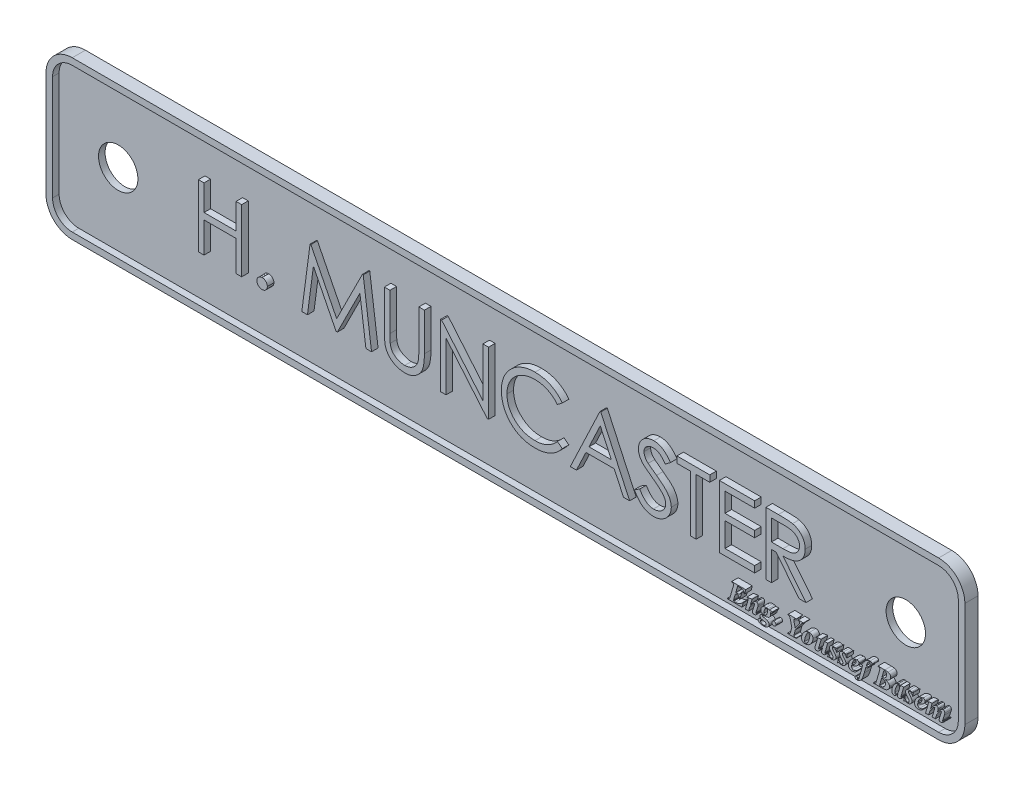
from build123d import *

# Parameters (mm, degrees)
BOSS_EXTRUDE1_DEPTH    = 1
SKETCH1_3_R            = 1.5
BOSS_EXTRUDE2_DEPTH    = 0.5
BOSS_EXTRUDE4_DEPTH    = 0.5
BOSS_EXTRUDE4_2_DEPTH  = 0.5
BOSS_EXTRUDE4_3_DEPTH  = 0.5
BOSS_EXTRUDE4_4_DEPTH  = 0.5
BOSS_EXTRUDE4_5_DEPTH  = 0.5
BOSS_EXTRUDE4_6_DEPTH  = 0.5
BOSS_EXTRUDE4_7_DEPTH  = 0.5
BOSS_EXTRUDE4_8_DEPTH  = 0.5
BOSS_EXTRUDE4_9_DEPTH  = 0.5
BOSS_EXTRUDE4_10_DEPTH = 0.5
BOSS_EXTRUDE4_11_DEPTH = 0.5
BOSS_EXTRUDE4_12_DEPTH = 0.5
BOSS_EXTRUDE4_13_DEPTH = 0.5
BOSS_EXTRUDE4_14_DEPTH = 0.5
BOSS_EXTRUDE4_15_DEPTH = 0.5
BOSS_EXTRUDE4_16_DEPTH = 0.5
BOSS_EXTRUDE4_17_DEPTH = 0.5
BOSS_EXTRUDE4_18_DEPTH = 0.5
BOSS_EXTRUDE4_19_DEPTH = 0.5
BOSS_EXTRUDE4_20_DEPTH = 0.5
BOSS_EXTRUDE4_21_DEPTH = 0.5
BOSS_EXTRUDE4_22_DEPTH = 0.5
BOSS_EXTRUDE4_23_DEPTH = 0.5
BOSS_EXTRUDE4_24_DEPTH = 0.5
BOSS_EXTRUDE4_25_DEPTH = 0.5
BOSS_EXTRUDE4_26_DEPTH = 0.5
BOSS_EXTRUDE4_27_DEPTH = 0.5


with BuildPart() as part:
    # Sketch1 → Boss-Extrude1 (new body)
    with BuildSketch(Plane.XY):
        with BuildLine():
            ThreePointArc((-35, 4), (-34.414213562, 5.414213562), (-33, 6))
            Line((-33, 6), (33, 6))
            ThreePointArc((33, 6), (34.414213562, 5.414213562), (35, 4))
            Line((35, 4), (35, -4))
            ThreePointArc((35, -4), (34.414213562, -5.414213562), (33, -6))
            Line((33, -6), (-33, -6))
            ThreePointArc((-33, -6), (-34.414213562, -5.414213562), (-35, -4))
            Line((-35, -4), (-35, 4))
        make_face()
        with BuildLine():
            Line((-33, -5.5), (33, -5.5))
            ThreePointArc((33, -5.5), (34.060660172, -5.060660172), (34.5, -4))
            Line((34.5, -4), (34.5, 4))
            ThreePointArc((34.5, 4), (34.060660172, 5.060660172), (33, 5.5))
            Line((33, 5.5), (-33, 5.5))
            ThreePointArc((-33, 5.5), (-34.060660172, 5.060660172), (-34.5, 4))
            Line((-34.5, 4), (-34.5, -4))
            ThreePointArc((-34.5, -4), (-34.060660172, -5.060660172), (-33, -5.5))
        make_face(mode=Mode.SUBTRACT)
    extrude(amount=BOSS_EXTRUDE1_DEPTH)

    # Sketch1<3> → Boss-Extrude2 (add)
    with BuildSketch(Plane.XY):
        with BuildLine():
            ThreePointArc((-33, -5.5), (-34.060660172, -5.060660172), (-34.5, -4))
            Line((-34.5, -4), (-34.5, 4))
            ThreePointArc((-34.5, 4), (-34.060660172, 5.060660172), (-33, 5.5))
            Line((-33, 5.5), (33, 5.5))
            ThreePointArc((33, 5.5), (34.060660172, 5.060660172), (34.5, 4))
            Line((34.5, 4), (34.5, -4))
            ThreePointArc((34.5, -4), (34.060660172, -5.060660172), (33, -5.5))
            Line((33, -5.5), (-33, -5.5))
        make_face()
        with Locations((-30, 0)):
            Circle(SKETCH1_3_R, mode=Mode.SUBTRACT)
        with Locations((30, 0)):
            Circle(SKETCH1_3_R, mode=Mode.SUBTRACT)
    extrude(amount=BOSS_EXTRUDE2_DEPTH)


with BuildPart() as body_2:
    # Sketch3 → Boss-Extrude4 (new body)
    with BuildSketch(Plane.XY.offset(0.5)):
        Polygon((-23.389423077, 2.7625), (-22.962019231, 2.7625), (-22.962019231, 0.808653846), (-20.519711538, 0.808653846), (-20.519711538, 2.7625), (-20.092307692, 2.7625), (-20.092307692, -2), (-20.519711538, -2), (-20.519711538, 0.320192308), (-22.962019231, 0.320192308), (-22.962019231, -2), (-23.389423077, -2), align=None)
    extrude(amount=BOSS_EXTRUDE4_DEPTH)


with BuildPart() as body_3:
    # Sketch3 → Boss-Extrude4 2 (new body)
    with BuildSketch(Plane.XY.offset(0.5)):
        with BuildLine():
            add(Edge.make_bspline(
                [(-18.535336538, -1.267307692), (-18.508815928, -1.268883626), (-18.456825373, -1.271973061), (-18.381660702, -1.293168463), (-18.313632254, -1.330803997), (-18.253036592, -1.380963707), (-18.203089565, -1.441781734), (-18.164112786, -1.509267595), (-18.143102017, -1.585061548), (-18.140035087, -1.637353356), (-18.138461538, -1.664182692)],
                knots=[0, 0, 0, 0, 1.020151414, 1.999887582, 2.974338812, 3.990962822, 5.007586832, 5.987933904, 6.967670073, 8, 8, 8, 8], degree=3))
            add(Edge.make_bspline(
                [(-18.138461538, -1.664182692), (-18.140088409, -1.690367366), (-18.143296575, -1.742003158), (-18.164064624, -1.817225434), (-18.203386614, -1.884753472), (-18.252692086, -1.946396738), (-18.313647234, -1.996662709), (-18.381821532, -2.033978046), (-18.456648922, -2.056691061), (-18.508786491, -2.059584344), (-18.535336538, -2.061057692)],
                knots=[0, 0, 0, 0, 1.009421747, 1.99056486, 2.972319754, 3.999869655, 5.017953583, 5.993804169, 6.978383603, 8, 8, 8, 8], degree=3))
            add(Edge.make_bspline(
                [(-18.535336538, -2.061057692), (-18.561905717, -2.059637655), (-18.613775714, -2.056865369), (-18.688323799, -2.033511694), (-18.756913281, -1.997012628), (-18.81785656, -1.946303012), (-18.867574981, -1.885070674), (-18.905165234, -1.816760372), (-18.927739686, -1.742218488), (-18.930708592, -1.690409778), (-18.932211538, -1.664182692)],
                knots=[0, 0, 0, 0, 1.022052826, 1.995314843, 2.982371812, 4.00089066, 5.028879526, 6.005146991, 6.990147033, 8, 8, 8, 8], degree=3))
            add(Edge.make_bspline(
                [(-18.932211538, -1.664182692), (-18.930766325, -1.637309429), (-18.927944723, -1.584842681), (-18.905117842, -1.509732467), (-18.867866639, -1.441467555), (-18.81751287, -1.381056494), (-18.756928024, -1.3304552), (-18.688489259, -1.29362775), (-18.613596171, -1.271801332), (-18.561875504, -1.26883155), (-18.535336538, -1.267307692)],
                knots=[0, 0, 0, 0, 1.032775665, 2.016367738, 2.991239715, 4.008302682, 5.025365648, 6.011011707, 6.979408107, 8, 8, 8, 8], degree=3))
        make_face()
    extrude(amount=BOSS_EXTRUDE4_2_DEPTH)


with BuildPart() as body_4:
    # Sketch3 → Boss-Extrude4 3 (new body)
    with BuildSketch(Plane.XY.offset(0.5)):
        Polygon((-15.512980769, -2), (-14.884277344, 2.7625), (-14.823219651, 2.7625), (-12.856971154, -1.145192308), (-10.896446815, 2.7625), (-10.835389123, 2.7625), (-10.200961538, -2), (-10.628365385, -2), (-11.086298077, 1.424000901), (-12.8044997, -2), (-12.901810397, -2), (-14.627644231, 1.434495192), (-15.082714844, -2), align=None)
    extrude(amount=BOSS_EXTRUDE4_3_DEPTH)


with BuildPart() as body_5:
    # Sketch3 → Boss-Extrude4 4 (new body)
    with BuildSketch(Plane.XY.offset(0.5)):
        with BuildLine():
            Line((-9.224038462, 2.7625), (-8.796634615, 2.7625))
            Line((-8.796634615, 2.7625), (-8.796634615, -0.090993089))
            add(Edge.make_bspline(
                [(-8.796634615, -0.090993089), (-8.796698221, -0.13138009), (-8.796818922, -0.208021385), (-8.79601268, -0.317107536), (-8.793754754, -0.41408899), (-8.79233123, -0.499339573), (-8.789164394, -0.572468098), (-8.786581694, -0.633870752), (-8.783260794, -0.683256792), (-8.779269659, -0.712077981), (-8.777554087, -0.724466647)],
                knots=[0, 0, 0, 0, 1.528628734, 2.90083645, 4.128790002, 5.200304208, 6.127813768, 6.898992206, 7.526736466, 8, 8, 8, 8], degree=3))
            add(Edge.make_bspline(
                [(-8.777554087, -0.724466647), (-8.770509044, -0.769161707), (-8.756815923, -0.85603342), (-8.72191853, -0.979733618), (-8.673181145, -1.091218924), (-8.61542829, -1.193968216), (-8.539319987, -1.285121596), (-8.44814732, -1.369093523), (-8.33768757, -1.442533729), (-8.214868675, -1.509686083), (-8.082491262, -1.563658928), (-7.947220932, -1.604471327), (-7.811091021, -1.629343687), (-7.719955596, -1.632223692), (-7.674699519, -1.633653846)],
                knots=[0, 0, 0, 0, 1.035780045, 2.013197591, 2.933192213, 3.817615948, 4.702609284, 5.640816605, 6.646850145, 7.73207398, 8.84249596, 9.914020372, 10.964143139, 12, 12, 12, 12], degree=3))
            add(Edge.make_bspline(
                [(-7.674699519, -1.633653846), (-7.635846037, -1.632192643), (-7.558363479, -1.629278675), (-7.4432383, -1.611233657), (-7.331115295, -1.578711816), (-7.221440799, -1.536747716), (-7.118637495, -1.481301886), (-7.022648026, -1.417251923), (-6.936972101, -1.342125695), (-6.858788182, -1.258985583), (-6.79070493, -1.165178213), (-6.731689199, -1.062746175), (-6.683348559, -0.950147956), (-6.659476834, -0.871016403), (-6.647213041, -0.830363582)],
                knots=[0, 0, 0, 0, 0.994687771, 1.983630487, 2.973142513, 3.978332533, 4.983357753, 5.956394766, 6.925816176, 7.893390482, 8.871859704, 9.88551698, 10.913711441, 12, 12, 12, 12], degree=3))
            add(Edge.make_bspline(
                [(-6.647213041, -0.830363582), (-6.643130728, -0.8135607), (-6.634033688, -0.776117109), (-6.625533245, -0.712814924), (-6.616679723, -0.638126182), (-6.610536683, -0.551514251), (-6.604547879, -0.453269356), (-6.60096502, -0.342879699), (-6.599308986, -0.22074612), (-6.598815481, -0.135514839), (-6.598557692, -0.090993089)],
                knots=[0, 0, 0, 0, 0.558680831, 1.244966039, 2.062412453, 2.990489873, 4.051219941, 5.244515665, 6.560634259, 8, 8, 8, 8], degree=3))
            Line((-6.598557692, -0.090993089), (-6.598557692, 2.7625))
            Line((-6.598557692, 2.7625), (-6.171153846, 2.7625))
            Line((-6.171153846, 2.7625), (-6.171153846, -0.113889724))
            add(Edge.make_bspline(
                [(-6.171153846, -0.113889724), (-6.171499631, -0.165730732), (-6.172174452, -0.266901612), (-6.178026308, -0.415153283), (-6.187356726, -0.555787161), (-6.200539446, -0.688822151), (-6.218006939, -0.813782203), (-6.237431436, -0.93176262), (-6.262168586, -1.041916513), (-6.291061178, -1.145102767), (-6.324090542, -1.243326627), (-6.366872962, -1.336547277), (-6.415075585, -1.427598657), (-6.472245523, -1.515103619), (-6.536486726, -1.599449608), (-6.609219192, -1.680125099), (-6.688037425, -1.758419301), (-6.774251683, -1.832323866), (-6.86644079, -1.900099245), (-6.964330518, -1.959695497), (-7.067168909, -2.010074063), (-7.174688641, -2.051543088), (-7.286935599, -2.082723311), (-7.403912614, -2.105957719), (-7.525885944, -2.119159774), (-7.608841423, -2.121121829), (-7.650848858, -2.122115385)],
                knots=[0, 0, 0, 0, 1.316592851, 2.569410997, 3.76748051, 4.895814652, 5.963796859, 6.97159953, 7.931736103, 8.829262218, 9.692595152, 10.560224239, 11.431080259, 12.30701507, 13.211635791, 14.121146779, 15.063487852, 16.031507147, 17.00238618, 17.966455255, 18.938106653, 19.907068911, 20.888905087, 21.893141452, 22.933117798, 24, 24, 24, 24], degree=3))
            add(Edge.make_bspline(
                [(-7.650848858, -2.122115385), (-7.696662887, -2.121047543), (-7.786549848, -2.118952442), (-7.918999147, -2.1069472), (-8.045973107, -2.084334314), (-8.168812782, -2.055541676), (-8.285845773, -2.015830948), (-8.398640067, -1.969433142), (-8.505263844, -1.912450156), (-8.607446858, -1.84904986), (-8.702458401, -1.777714906), (-8.789676653, -1.699963455), (-8.869245606, -1.617041013), (-8.939824082, -1.528049801), (-9.002581428, -1.433681943), (-9.056642897, -1.333670477), (-9.103061276, -1.228054126), (-9.127018783, -1.154639235), (-9.139130108, -1.117525541)],
                knots=[0, 0, 0, 0, 1.13879206, 2.234305948, 3.301075583, 4.341971843, 5.366689343, 6.369221514, 7.369726634, 8.367512178, 9.355451585, 10.318319045, 11.268648973, 12.207971039, 13.137398894, 14.081662264, 15.030215811, 16, 16, 16, 16], degree=3))
            add(Edge.make_bspline(
                [(-9.139130108, -1.117525541), (-9.146174741, -1.092171931), (-9.161454707, -1.037179385), (-9.177817702, -0.946165985), (-9.191573273, -0.841370686), (-9.204507622, -0.722786316), (-9.212139811, -0.590320962), (-9.218831041, -0.444032044), (-9.2240856, -0.283742675), (-9.224054614, -0.172089923), (-9.224038462, -0.113889724)],
                knots=[0, 0, 0, 0, 0.625038921, 1.35572334, 2.194682327, 3.136881307, 4.189498639, 5.346923369, 6.617055217, 8, 8, 8, 8], degree=3))
            Line((-9.224038462, -0.113889724), (-9.224038462, 2.7625))
        make_face()
    extrude(amount=BOSS_EXTRUDE4_4_DEPTH)


with BuildPart() as body_6:
    # Sketch3 → Boss-Extrude4 5 (new body)
    with BuildSketch(Plane.XY.offset(0.5)):
        Polygon((-4.95, -2), (-4.95, 2.7625), (-4.860321514, 2.7625), (-1.713942308, -0.985869892), (-1.713942308, 2.7625), (-1.286538462, 2.7625), (-1.286538462, -2), (-1.383849159, -2), (-4.522596154, 1.739783654), (-4.522596154, -2), align=None)
    extrude(amount=BOSS_EXTRUDE4_5_DEPTH)


with BuildPart() as body_7:
    # Sketch3 → Boss-Extrude4 6 (new body)
    with BuildSketch(Plane.XY.offset(0.5)):
        with BuildLine():
            Line((4.330769231, 1.888611779), (3.956790865, 1.602403846))
            add(Edge.make_bspline(
                [(3.956790865, 1.602403846), (3.930112853, 1.634198255), (3.877116506, 1.697358415), (3.791855234, 1.786049153), (3.702998355, 1.869141526), (3.610579837, 1.94703137), (3.512936178, 2.016994897), (3.412432734, 2.082678077), (3.307388251, 2.141553106), (3.162129641, 2.21294024), (2.972108819, 2.287434116), (2.73290227, 2.349895298), (2.483196096, 2.389656969), (2.312837934, 2.393963414), (2.226186899, 2.396153846)],
                knots=[0, 0, 0, 0, 0.757959112, 1.505699292, 2.245454638, 2.979532153, 3.711538275, 4.438200793, 5.171680507, 5.909471876, 7.393775596, 8.890124382, 10.418191784, 12, 12, 12, 12], degree=3))
            add(Edge.make_bspline(
                [(2.226186899, 2.396153846), (2.178448552, 2.395604169), (2.083414916, 2.394509915), (1.942378958, 2.380073927), (1.803976556, 2.35978403), (1.668297739, 2.329677787), (1.535515214, 2.291615044), (1.404760909, 2.246132606), (1.277927915, 2.189860485), (1.153261669, 2.127664603), (1.033819243, 2.057414401), (0.920805053, 1.980788019), (0.814631282, 1.898642927), (0.715213942, 1.810671243), (0.622451398, 1.717269146), (0.537015807, 1.617441239), (0.459202802, 1.511506674), (0.387469993, 1.400862359), (0.323226953, 1.285830578), (0.269438081, 1.165985571), (0.221806111, 1.043379631), (0.184115356, 0.916627516), (0.154282353, 0.78662111), (0.133697925, 0.653011502), (0.119426113, 0.516077816), (0.1183373, 0.42326443), (0.117788462, 0.376479868)],
                knots=[0, 0, 0, 0, 1.054917814, 2.100044995, 3.131103042, 4.146048494, 5.169673617, 6.183595914, 7.203665975, 8.234915748, 9.262203917, 10.264457458, 11.251630812, 12.227803204, 13.197192746, 14.159520551, 15.12972552, 16.100847026, 17.073214652, 18.039054194, 19.002613845, 19.979014051, 20.95965708, 21.949030935, 22.966165397, 24, 24, 24, 24], degree=3))
            add(Edge.make_bspline(
                [(0.117788462, 0.376479868), (0.119505437, 0.306088322), (0.12287649, 0.167883858), (0.152877973, -0.034550437), (0.198468829, -0.228480354), (0.266797882, -0.412693639), (0.351052019, -0.589461798), (0.457515137, -0.755793952), (0.580818354, -0.914203634), (0.722706046, -1.060947074), (0.878379674, -1.194996107), (1.045404511, -1.313038863), (1.223364559, -1.411438757), (1.410294903, -1.493321027), (1.607634008, -1.556263217), (1.815027007, -1.600573685), (2.032022829, -1.629478223), (2.180299048, -1.632245492), (2.255761719, -1.633653846)],
                knots=[0, 0, 0, 0, 1.029171465, 2.020641659, 2.987623507, 3.938342917, 4.889210282, 5.84687017, 6.821220943, 7.821438502, 8.827599549, 9.822697543, 10.807740252, 11.797342354, 12.80366471, 13.83203677, 14.896651826, 16, 16, 16, 16], degree=3))
            add(Edge.make_bspline(
                [(2.255761719, -1.633653846), (2.338905021, -1.631355899), (2.502550928, -1.626832991), (2.742537421, -1.588516298), (2.972274659, -1.526388917), (3.191775, -1.439442101), (3.400419644, -1.326413977), (3.598535099, -1.189392937), (3.786288594, -1.027075598), (3.899188803, -0.903137485), (3.956790865, -0.839903846)],
                knots=[0, 0, 0, 0, 1.028121516, 2.023589091, 2.998037872, 3.967518031, 4.937445131, 5.927275754, 6.942489185, 8, 8, 8, 8], degree=3))
            Line((3.956790865, -0.839903846), (4.330769231, -1.1232497))
            add(Edge.make_bspline(
                [(4.330769231, -1.1232497), (4.300672803, -1.162082379), (4.240624107, -1.239561731), (4.143390162, -1.348788593), (4.040959268, -1.451528013), (3.932570606, -1.546951669), (3.819471039, -1.636968995), (3.699629786, -1.719022558), (3.574622281, -1.794257655), (3.444872079, -1.863146434), (3.310517038, -1.924265974), (3.171718146, -1.976590565), (3.029073685, -2.021664075), (2.882577132, -2.058746175), (2.73192462, -2.087690043), (2.577659796, -2.107038957), (2.419449716, -2.120294919), (2.312713354, -2.121503119), (2.258623798, -2.122115385)],
                knots=[0, 0, 0, 0, 0.986787822, 1.968848986, 2.935600012, 3.899624008, 4.868462664, 5.837806735, 6.815139263, 7.798259679, 8.787526145, 9.778297419, 10.776456485, 11.791383307, 12.812564526, 13.85620153, 14.913611965, 16, 16, 16, 16], degree=3))
            add(Edge.make_bspline(
                [(2.258623798, -2.122115385), (2.207401523, -2.121758888), (2.106115816, -2.121053959), (1.956575014, -2.109634617), (1.810992763, -2.094054796), (1.669785147, -2.070595904), (1.532181589, -2.042913069), (1.399429507, -2.005804681), (1.270222596, -1.964235994), (1.145079961, -1.915379565), (1.023895155, -1.860248617), (0.907059041, -1.797939388), (0.794625352, -1.728975851), (0.68548869, -1.654878141), (0.581261264, -1.573266169), (0.48103986, -1.485273356), (0.38426249, -1.391196277), (0.324387408, -1.323358066), (0.294283353, -1.2892503)],
                knots=[0, 0, 0, 0, 1.114604814, 2.203992996, 3.262667896, 4.300477797, 5.318619304, 6.316056647, 7.298880507, 8.271930387, 9.238335007, 10.195173496, 11.151986948, 12.108099108, 13.064862484, 14.031167946, 15.010108607, 16, 16, 16, 16], degree=3))
            add(Edge.make_bspline(
                [(0.294283353, -1.2892503), (0.246065567, -1.230003183), (0.150212122, -1.11222423), (0.027576817, -0.921335092), (-0.077398964, -0.722033707), (-0.16227477, -0.513273019), (-0.228626918, -0.295521467), (-0.274593473, -0.068669284), (-0.304463334, 0.167071665), (-0.30787912, 0.327413867), (-0.309615385, 0.408916767)],
                knots=[0, 0, 0, 0, 0.994628077, 1.977248131, 2.950237994, 3.925870899, 4.908910175, 5.911660606, 6.938484602, 8, 8, 8, 8], degree=3))
            add(Edge.make_bspline(
                [(-0.309615385, 0.408916767), (-0.307499211, 0.494581152), (-0.30333577, 0.663120481), (-0.26796292, 0.910462896), (-0.211059486, 1.147433193), (-0.130237292, 1.373589002), (-0.027768224, 1.590119848), (0.098814418, 1.79537163), (0.248040065, 1.99065699), (0.418738363, 2.173012776), (0.605928201, 2.339753824), (0.806387016, 2.486447265), (1.019722451, 2.608527171), (1.243584242, 2.710575521), (1.479648687, 2.789013165), (1.727412128, 2.843922323), (1.986409009, 2.878099542), (2.163114667, 2.882420093), (2.252899639, 2.884615385)],
                knots=[0, 0, 0, 0, 1.032925535, 2.032216505, 3.007276963, 3.968222605, 4.92396291, 5.891752235, 6.871517503, 7.883894988, 8.900124299, 9.891468569, 10.874487609, 11.85992873, 12.854644235, 13.869047385, 14.917252991, 16, 16, 16, 16], degree=3))
            add(Edge.make_bspline(
                [(2.252899639, 2.884615385), (2.307620046, 2.883959332), (2.41593358, 2.882660743), (2.576161296, 2.869997742), (2.732156748, 2.848888157), (2.884027406, 2.820155219), (3.032512109, 2.784494542), (3.176476008, 2.73803935), (3.316763864, 2.684921785), (3.452490907, 2.623746158), (3.583005927, 2.555075342), (3.708268274, 2.479670511), (3.827282957, 2.397625147), (3.940887426, 2.309637041), (4.04718127, 2.213844715), (4.149182425, 2.112882987), (4.243426963, 2.003843747), (4.301601847, 1.927092748), (4.330769231, 1.888611779)],
                knots=[0, 0, 0, 0, 1.096760587, 2.17092713, 3.219439832, 4.250915756, 5.268269357, 6.278326846, 7.281116186, 8.274029601, 9.260640565, 10.235837813, 11.203064059, 12.156899882, 13.114053108, 14.069676657, 15.032185724, 16, 16, 16, 16], degree=3))
        make_face()
    extrude(amount=BOSS_EXTRUDE4_6_DEPTH)


with BuildPart() as body_8:
    # Sketch3 → Boss-Extrude4 7 (new body)
    with BuildSketch(Plane.XY.offset(0.5)):
        Polygon((7.261538462, 2.7625), (9.459615385, -2), (8.995004507, -2), (8.290932993, -0.473557692), (6.131971154, -0.473557692), (5.408819111, -2), (4.941346154, -2), (7.200480769, 2.7625), align=None)
        Polygon((7.226239483, 1.833278245), (6.364753606, 0.014903846), (8.065782752, 0.014903846), align=None, mode=Mode.SUBTRACT)
    extrude(amount=BOSS_EXTRUDE4_7_DEPTH)


with BuildPart() as body_9:
    # Sketch3 → Boss-Extrude4 8 (new body)
    with BuildSketch(Plane.XY.offset(0.5)):
        with BuildLine():
            Line((9.825961538, -1.081272536), (10.228560697, -0.839903846))
            add(Edge.make_bspline(
                [(10.228560697, -0.839903846), (10.266005156, -0.902584313), (10.337747293, -1.022677668), (10.457423964, -1.184953787), (10.581429818, -1.322878722), (10.710683161, -1.435650106), (10.844395041, -1.524435198), (10.983438342, -1.587303235), (11.127344506, -1.626513544), (11.225280313, -1.631276162), (11.274173678, -1.633653846)],
                knots=[0, 0, 0, 0, 1.272034388, 2.437168799, 3.508375237, 4.49857839, 5.41946034, 6.295179144, 7.148887113, 8, 8, 8, 8], degree=3))
            add(Edge.make_bspline(
                [(11.274173678, -1.633653846), (11.315929727, -1.632490881), (11.398711194, -1.6301853), (11.520579817, -1.60803178), (11.638937198, -1.573997419), (11.751343951, -1.525255366), (11.856249055, -1.466284069), (11.948242452, -1.395055878), (12.027770913, -1.315309576), (12.092825458, -1.226342464), (12.142736506, -1.130660915), (12.181097856, -1.032450067), (12.202386331, -0.930167123), (12.2055932, -0.861300743), (12.207211538, -0.826547476)],
                knots=[0, 0, 0, 0, 1.095163259, 2.171163733, 3.241058638, 4.321873601, 5.38011039, 6.391990106, 7.366004449, 8.327778327, 9.272591725, 10.192022065, 11.087607919, 12, 12, 12, 12], degree=3))
            add(Edge.make_bspline(
                [(12.207211538, -0.826547476), (12.205205423, -0.786895105), (12.201127283, -0.706287631), (12.166658376, -0.587361674), (12.112434937, -0.469669999), (12.062411482, -0.396870062), (12.036440805, -0.359074519)],
                knots=[0, 0, 0, 0, 0.938893495, 1.908633276, 2.914225137, 4, 4, 4, 4], degree=3))
            add(Edge.make_bspline(
                [(12.036440805, -0.359074519), (12.015117577, -0.33179652), (11.970352126, -0.274529773), (11.89339351, -0.189287506), (11.80308819, -0.1013603), (11.702526567, -0.007390655), (11.588045472, 0.088250954), (11.463230532, 0.19012529), (11.324895067, 0.29435815), (11.227876823, 0.364261534), (11.177817007, 0.400330529)],
                knots=[0, 0, 0, 0, 0.722233717, 1.516239348, 2.393582979, 3.351407094, 4.387010283, 5.505090956, 6.712668013, 8, 8, 8, 8], degree=3))
            add(Edge.make_bspline(
                [(11.177817007, 0.400330529), (11.12771007, 0.436020143), (11.03190942, 0.504255967), (10.897935421, 0.605526153), (10.778132062, 0.698114418), (10.673031829, 0.782892378), (10.582680949, 0.859871529), (10.50636745, 0.928312654), (10.446035342, 0.990066713), (10.412486142, 1.030127968), (10.397423377, 1.048114483)],
                knots=[0, 0, 0, 0, 1.452282411, 2.77665338, 3.964542531, 5.026858415, 5.96415736, 6.766646006, 7.446254459, 8, 8, 8, 8], degree=3))
            add(Edge.make_bspline(
                [(10.397423377, 1.048114483), (10.376369664, 1.076146608), (10.334964711, 1.131275545), (10.280310254, 1.217442583), (10.233856607, 1.305648526), (10.19744072, 1.396130399), (10.166775365, 1.487617927), (10.146149752, 1.581304801), (10.133234672, 1.676770636), (10.131912077, 1.74101472), (10.13125, 1.773174579)],
                knots=[0, 0, 0, 0, 1.068054152, 2.10047183, 3.106115577, 4.101338837, 5.06977816, 6.043150881, 7.020423561, 8, 8, 8, 8], degree=3))
            add(Edge.make_bspline(
                [(10.13125, 1.773174579), (10.133026017, 1.823561523), (10.136540088, 1.923258424), (10.166258792, 2.068896804), (10.213166551, 2.207943321), (10.278882095, 2.339021383), (10.363596565, 2.458717949), (10.461630551, 2.568409873), (10.578395466, 2.660623551), (10.706510286, 2.741194244), (10.846740564, 2.804257807), (10.993685329, 2.851829712), (11.14757813, 2.878784452), (11.25181311, 2.882652643), (11.304702524, 2.884615385)],
                knots=[0, 0, 0, 0, 1.005424448, 1.989358655, 2.955360095, 3.929531133, 4.905563448, 5.876582895, 6.856512386, 7.866279853, 8.892233794, 9.918561126, 10.94386622, 12, 12, 12, 12], degree=3))
            add(Edge.make_bspline(
                [(11.304702524, 2.884615385), (11.360823961, 2.882679698), (11.472431586, 2.878830236), (11.636600697, 2.845360024), (11.794662243, 2.789978038), (11.921811828, 2.727128472), (12.021324622, 2.664356795), (12.097215376, 2.60717982), (12.174119478, 2.541355119), (12.25265726, 2.466707359), (12.331497943, 2.382551601), (12.411811998, 2.289464199), (12.493787235, 2.188014029), (12.546522888, 2.11559069), (12.573557692, 2.078463041)],
                knots=[0, 0, 0, 0, 1.286793592, 2.559021753, 3.825965368, 5.121522368, 5.803751409, 6.523245864, 7.299691795, 8.125521123, 9.008227632, 9.944561021, 10.946284179, 12, 12, 12, 12], degree=3))
            Line((12.573557692, 2.078463041), (12.187176983, 1.785576923))
            add(Edge.make_bspline(
                [(12.187176983, 1.785576923), (12.163846268, 1.81563332), (12.118916765, 1.873514912), (12.050704856, 1.954574452), (11.986412946, 2.028619733), (11.923071152, 2.092934068), (11.864024818, 2.151039471), (11.806715557, 2.200786855), (11.7519681, 2.242663647), (11.682956876, 2.287354348), (11.596255266, 2.331654448), (11.487419165, 2.369140872), (11.373682126, 2.391667581), (11.296217163, 2.394646032), (11.257001202, 2.396153846)],
                knots=[0, 0, 0, 0, 1.181633172, 2.275549214, 3.290209073, 4.226197932, 5.078386478, 5.862611352, 6.581680152, 7.217281963, 8.414376989, 9.595101626, 10.782541182, 12, 12, 12, 12], degree=3))
            add(Edge.make_bspline(
                [(11.257001202, 2.396153846), (11.207802505, 2.394505069), (11.112927454, 2.391325557), (10.978230025, 2.356600148), (10.856998649, 2.301924117), (10.75283248, 2.225295522), (10.666104665, 2.134507314), (10.603368308, 2.030033229), (10.565608263, 1.914668602), (10.561000504, 1.834193706), (10.558653846, 1.793209135)],
                knots=[0, 0, 0, 0, 1.14458467, 2.207223713, 3.21896685, 4.227309161, 5.202851033, 6.127160689, 7.046193047, 8, 8, 8, 8], degree=3))
            add(Edge.make_bspline(
                [(10.558653846, 1.793209135), (10.559188779, 1.76769373), (10.56025952, 1.716621198), (10.575193084, 1.641167656), (10.594378242, 1.565904726), (10.62478018, 1.491170783), (10.666751826, 1.415658816), (10.721867797, 1.338068523), (10.79128234, 1.257716019), (10.844454989, 1.205454557), (10.872528546, 1.177862079)],
                knots=[0, 0, 0, 0, 0.858281714, 1.717966888, 2.583508476, 3.4729293, 4.427298488, 5.488583878, 6.674047936, 8, 8, 8, 8], degree=3))
            add(Edge.make_bspline(
                [(10.872528546, 1.177862079), (10.882953485, 1.168558841), (10.907720753, 1.146456475), (10.952999781, 1.110271979), (11.012793374, 1.065636778), (11.085540155, 1.010409037), (11.172581458, 0.946344619), (11.273926854, 0.874262668), (11.388446654, 0.791823168), (11.469711118, 0.734186658), (11.512680288, 0.703710938)],
                knots=[0, 0, 0, 0, 0.420754252, 0.999615792, 1.744751191, 2.668019286, 3.750313428, 4.999500688, 6.413464383, 8, 8, 8, 8], degree=3))
            add(Edge.make_bspline(
                [(11.512680288, 0.703710938), (11.564368263, 0.666098945), (11.664454863, 0.593268534), (11.806863927, 0.483845769), (11.935987287, 0.376828627), (12.052278289, 0.272900526), (12.156885797, 0.172849799), (12.248649267, 0.075472757), (12.32850371, -0.018532968), (12.414472576, -0.139054938), (12.502317323, -0.287074913), (12.577757374, -0.468428516), (12.625325697, -0.650487081), (12.631546223, -0.772851812), (12.634615385, -0.833225661)],
                knots=[0, 0, 0, 0, 1.163667725, 2.253281268, 3.268753668, 4.215851969, 5.092017293, 5.902905408, 6.650798638, 7.335211899, 8.59617414, 9.77448103, 10.901945474, 12, 12, 12, 12], degree=3))
            add(Edge.make_bspline(
                [(12.634615385, -0.833225661), (12.633721207, -0.875922651), (12.631950217, -0.960487483), (12.611592688, -1.08465957), (12.581766287, -1.205260861), (12.53681205, -1.320800624), (12.481943753, -1.433392605), (12.412321108, -1.540083355), (12.331620295, -1.643234205), (12.239045779, -1.740094598), (12.137746176, -1.829012101), (12.030680149, -1.908109145), (11.917672456, -1.974060685), (11.799336146, -2.027878081), (11.675644038, -2.06996976), (11.546637732, -2.100467271), (11.412104576, -2.119184864), (11.320663921, -2.121127639), (11.274173678, -2.122115385)],
                knots=[0, 0, 0, 0, 0.983748083, 1.948392443, 2.894712957, 3.844097841, 4.80183111, 5.778335162, 6.776009319, 7.81870978, 8.863265674, 9.881300176, 10.883814829, 11.87499822, 12.874611388, 13.892143829, 14.928324115, 16, 16, 16, 16], degree=3))
            add(Edge.make_bspline(
                [(11.274173678, -2.122115385), (11.238202729, -2.121419813), (11.166713848, -2.120037428), (11.060973446, -2.107816472), (10.95736922, -2.090525734), (10.857201214, -2.063074589), (10.759178879, -2.029768417), (10.663728535, -1.988758757), (10.570803923, -1.939613565), (10.479884283, -1.883422835), (10.391200853, -1.818029976), (10.305585434, -1.741866039), (10.220228935, -1.65703162), (10.137650728, -1.561222961), (10.056180485, -1.455987926), (9.977424506, -1.340341931), (9.899752598, -1.214914888), (9.851017979, -1.12665204), (9.825961538, -1.081272536)],
                knots=[0, 0, 0, 0, 0.915332311, 1.819136955, 2.706846663, 3.586547465, 4.459518054, 5.340707479, 6.227863349, 7.133153174, 8.059268498, 9.028702269, 10.047606654, 11.120612155, 12.245963614, 13.433783089, 14.680604001, 16, 16, 16, 16], degree=3))
        make_face()
    extrude(amount=BOSS_EXTRUDE4_8_DEPTH)


with BuildPart() as body_10:
    # Sketch3 → Boss-Extrude4 9 (new body)
    with BuildSketch(Plane.XY.offset(0.5)):
        Polygon((13.062019231, 2.274038462), (13.062019231, 2.7625), (15.565384615, 2.7625), (15.565384615, 2.274038462), (14.527403846, 2.274038462), (14.527403846, -2), (14.1, -2), (14.1, 2.274038462), align=None)
    extrude(amount=BOSS_EXTRUDE4_9_DEPTH)


with BuildPart() as body_11:
    # Sketch3 → Boss-Extrude4 10 (new body)
    with BuildSketch(Plane.XY.offset(0.5)):
        Polygon((16.298076923, 2.7625), (18.984615385, 2.7625), (18.984615385, 2.274038462), (16.725480769, 2.274038462), (16.725480769, 0.808653846), (18.984615385, 0.808653846), (18.984615385, 0.320192308), (16.725480769, 0.320192308), (16.725480769, -1.511538462), (18.984615385, -1.511538462), (18.984615385, -2), (16.298076923, -2), align=None)
    extrude(amount=BOSS_EXTRUDE4_10_DEPTH)


with BuildPart() as body_12:
    # Sketch3 → Boss-Extrude4 11 (new body)
    with BuildSketch(Plane.XY.offset(0.5)):
        with BuildLine():
            Line((19.839423077, 2.7625), (20.792495493, 2.7625))
            add(Edge.make_bspline(
                [(20.792495493, 2.7625), (20.856096814, 2.762288292), (20.978218396, 2.761881789), (21.153169882, 2.759615162), (21.312138182, 2.753118628), (21.455040178, 2.747528019), (21.581873247, 2.737333628), (21.693026311, 2.727590033), (21.787987428, 2.714835159), (21.845471961, 2.702989565), (21.871499399, 2.697626202)],
                knots=[0, 0, 0, 0, 1.410062039, 2.707475311, 3.878576406, 4.937260626, 5.877586885, 6.699081471, 7.410979367, 8, 8, 8, 8], degree=3))
            add(Edge.make_bspline(
                [(21.871499399, 2.697626202), (21.906342698, 2.689017282), (21.975285995, 2.671983094), (22.074550192, 2.635979137), (22.169139325, 2.594314576), (22.258660479, 2.545378228), (22.342665252, 2.488806831), (22.422019811, 2.425576993), (22.497084245, 2.356034688), (22.56482282, 2.278426565), (22.628693458, 2.197006171), (22.682562268, 2.108962845), (22.728998657, 2.016894838), (22.765969967, 1.919865816), (22.795739638, 1.818816762), (22.816730343, 1.712832364), (22.829318566, 1.602395465), (22.830600162, 1.527069168), (22.83125, 1.4888747)],
                knots=[0, 0, 0, 0, 1.027469482, 2.033020251, 3.019912614, 3.986113645, 4.951240523, 5.91722682, 6.890402269, 7.87763091, 8.8651537, 9.85103654, 10.82876324, 11.815024772, 12.821070561, 13.842952187, 14.906261191, 16, 16, 16, 16], degree=3))
            add(Edge.make_bspline(
                [(22.83125, 1.4888747), (22.829251113, 1.425417646), (22.825350768, 1.3015965), (22.788985537, 1.121899372), (22.729418201, 0.954273912), (22.64733544, 0.79893118), (22.542806082, 0.658899194), (22.41717842, 0.535903611), (22.27038237, 0.432979301), (22.133726765, 0.36160602), (22.013012086, 0.31589567), (21.913634614, 0.283733338), (21.80523062, 0.258884021), (21.688838747, 0.236622556), (21.56397463, 0.219815429), (21.430937541, 0.207505599), (21.289632599, 0.199812054), (21.192560508, 0.198666326), (21.142623197, 0.198076923)],
                knots=[0, 0, 0, 0, 1.260483769, 2.459530307, 3.627416485, 4.787058657, 5.939039949, 7.08810263, 8.267026773, 9.491475466, 10.141966685, 10.831826277, 11.566392101, 12.351337768, 13.187381173, 14.07005841, 15.007169909, 16, 16, 16, 16], degree=3))
            Line((21.142623197, 0.198076923), (22.892307692, -2))
            Line((22.892307692, -2), (22.363777043, -2))
            Line((22.363777043, -2), (20.614092548, 0.198076923))
            Line((20.614092548, 0.198076923), (20.266826923, 0.198076923))
            Line((20.266826923, 0.198076923), (20.266826923, -2))
            Line((20.266826923, -2), (19.839423077, -2))
            Line((19.839423077, -2), (19.839423077, 2.7625))
        make_face()
        with BuildLine():
            Line((20.266826923, 2.274038462), (20.266826923, 0.686538462))
            Line((20.266826923, 0.686538462), (21.138807091, 0.679860276))
            add(Edge.make_bspline(
                [(21.138807091, 0.679860276), (21.179519716, 0.679842265), (21.258432377, 0.679807354), (21.372597211, 0.685241742), (21.478896363, 0.691423901), (21.576923243, 0.700879974), (21.666721644, 0.713066629), (21.748246681, 0.72831069), (21.821631434, 0.746070818), (21.907218374, 0.773559459), (22.002790225, 0.817110505), (22.106655533, 0.880472844), (22.195105143, 0.960168681), (22.269832663, 1.05130042), (22.32988021, 1.151498316), (22.372214827, 1.259561304), (22.39907865, 1.372761299), (22.402247136, 1.450564368), (22.403846154, 1.489828726)],
                knots=[0, 0, 0, 0, 1.146690395, 2.22261258, 3.21895312, 4.145990853, 4.996080663, 5.770904154, 6.481378293, 7.121626537, 8.300444488, 9.431385265, 10.535395872, 11.636531494, 12.74115979, 13.810798291, 14.895190096, 16, 16, 16, 16], degree=3))
            add(Edge.make_bspline(
                [(22.403846154, 1.489828726), (22.402210411, 1.528128171), (22.398968964, 1.604023696), (22.372504747, 1.715134059), (22.327751696, 1.820000159), (22.267441794, 1.918195405), (22.193964372, 2.007329996), (22.10780692, 2.083594157), (22.011325208, 2.146526465), (21.921149041, 2.186741532), (21.840548202, 2.211397476), (21.770567129, 2.228748166), (21.691494011, 2.242687962), (21.602944905, 2.253856787), (21.505297829, 2.263456551), (21.39805905, 2.269922364), (21.281940074, 2.273751229), (21.201458, 2.273940489), (21.159795673, 2.274038462)],
                knots=[0, 0, 0, 0, 1.101028733, 2.181837193, 3.264309656, 4.369019818, 5.486613113, 6.575447106, 7.666700264, 8.788928104, 9.402425223, 10.0903467, 10.862060571, 11.710948788, 12.657782767, 13.684531032, 14.801375019, 16, 16, 16, 16], degree=3))
            Line((21.159795673, 2.274038462), (20.266826923, 2.274038462))
        make_face(mode=Mode.SUBTRACT)
    extrude(amount=BOSS_EXTRUDE4_11_DEPTH)


with BuildPart() as body_13:
    # Sketch3 → Boss-Extrude4 12 (new body)
    with BuildSketch(Plane.XY.offset(0.5)):
        with BuildLine():
            Line((17.689085665, -3.511919188), (17.544076985, -4.017474744))
            Line((17.544076985, -4.017474744), (17.586676811, -4.017474744))
            add(Edge.make_bspline(
                [(17.586676811, -4.017474744), (17.600221823, -4.017302949), (17.626390924, -4.016971041), (17.664230921, -4.01470149), (17.699167505, -4.011117038), (17.731323439, -4.006122782), (17.760562572, -3.999445509), (17.787036991, -3.991179138), (17.810850229, -3.981878355), (17.831867552, -3.970193581), (17.851293599, -3.956942155), (17.869447252, -3.941351813), (17.887193984, -3.923791727), (17.90371247, -3.903554693), (17.91983627, -3.881296536), (17.93512763, -3.856606492), (17.949368172, -3.829524648), (17.958211974, -3.810532459), (17.962740179, -3.800808077)],
                knots=[0, 0, 0, 0, 1.384600422, 2.675062164, 3.873631336, 4.973617757, 5.999665876, 6.936150921, 7.807299455, 8.607507698, 9.388783101, 10.207317138, 11.050213981, 11.93765297, 12.874138015, 13.858493481, 14.903505675, 16, 16, 16, 16], degree=3))
            Line((17.962740179, -3.800808077), (17.99885129, -3.800808077))
            Line((17.99885129, -3.800808077), (17.845379068, -4.306363633))
            Line((17.845379068, -4.306363633), (17.809267957, -4.306363633))
            add(Edge.make_bspline(
                [(17.809267957, -4.306363633), (17.810680123, -4.298666347), (17.813357763, -4.284071354), (17.815695834, -4.263130625), (17.817642813, -4.244521014), (17.817895599, -4.232829119), (17.818013616, -4.227370577)],
                knots=[0, 0, 0, 0, 1.179789964, 2.237025734, 3.176928258, 4, 4, 4, 4], degree=3))
            add(Edge.make_bspline(
                [(17.818013616, -4.227370577), (17.817761085, -4.219338065), (17.817269915, -4.203714978), (17.811392422, -4.181570623), (17.802346428, -4.161542521), (17.789353506, -4.144260893), (17.773717787, -4.129393614), (17.756093861, -4.116459196), (17.736124045, -4.106264558), (17.721787939, -4.101458189), (17.71447629, -4.099006862)],
                knots=[0, 0, 0, 0, 1.079935595, 2.100454703, 3.064397626, 4.025085809, 4.993102509, 5.964018586, 6.961616063, 8, 8, 8, 8], degree=3))
            add(Edge.make_bspline(
                [(17.71447629, -4.099006862), (17.708194792, -4.097581069), (17.693136741, -4.09416315), (17.666106104, -4.091467432), (17.63117847, -4.089954136), (17.60520555, -4.089788269), (17.590908582, -4.089696966)],
                knots=[0, 0, 0, 0, 0.621906755, 1.490839323, 2.618815627, 4, 4, 4, 4], degree=3))
            Line((17.590908582, -4.089696966), (17.522636012, -4.089696966))
            Line((17.522636012, -4.089696966), (17.395118651, -4.526979952))
            add(Edge.make_bspline(
                [(17.395118651, -4.526979952), (17.392707815, -4.535992037), (17.388256739, -4.552630855), (17.382935598, -4.575915892), (17.380041394, -4.595559158), (17.379345784, -4.607471628), (17.379037922, -4.612743841)],
                knots=[0, 0, 0, 0, 1.279992299, 2.363222322, 3.275595991, 4, 4, 4, 4], degree=3))
            add(Edge.make_bspline(
                [(17.379037922, -4.612743841), (17.379306768, -4.616268817), (17.379833735, -4.623178151), (17.384152466, -4.632860761), (17.390741455, -4.641578952), (17.396769743, -4.645989673), (17.399914658, -4.648290716)],
                knots=[0, 0, 0, 0, 0.981137765, 1.923136175, 2.916514593, 4, 4, 4, 4], degree=3))
            add(Edge.make_bspline(
                [(17.399914658, -4.648290716), (17.406217237, -4.651374336), (17.420521997, -4.658373131), (17.447133179, -4.663352563), (17.48000908, -4.667127741), (17.504278084, -4.66735202), (17.517557887, -4.667474744)],
                knots=[0, 0, 0, 0, 0.69710061, 1.582186851, 2.67699213, 4, 4, 4, 4], degree=3))
            add(Edge.make_bspline(
                [(17.517557887, -4.667474744), (17.531294487, -4.667257481), (17.558715104, -4.666823788), (17.599500543, -4.663343072), (17.639726822, -4.657735678), (17.679152366, -4.649747758), (17.718134203, -4.639964687), (17.756285367, -4.627428101), (17.794076331, -4.613123245), (17.831020774, -4.59607152), (17.867327736, -4.576883577), (17.903076884, -4.555743921), (17.937832693, -4.531974676), (17.971551522, -4.505652977), (18.004688219, -4.477419389), (18.036933374, -4.44685629), (18.068258898, -4.413863219), (18.088111452, -4.390438675), (18.098156846, -4.378585855)],
                knots=[0, 0, 0, 0, 0.982196594, 1.960633459, 2.924987342, 3.885111377, 4.836006194, 5.797260008, 6.755167698, 7.724129753, 8.704782681, 9.690862262, 10.692503861, 11.71346375, 12.748501048, 13.804538139, 14.889096214, 16, 16, 16, 16], degree=3))
            Line((18.098156846, -4.378585855), (18.134267957, -4.378585855))
            Line((18.134267957, -4.378585855), (18.007879068, -4.739696966))
            Line((18.007879068, -4.739696966), (16.906490179, -4.739696966))
            Line((16.906490179, -4.739696966), (16.906490179, -4.703585855))
            add(Edge.make_bspline(
                [(16.906490179, -4.703585855), (16.920902593, -4.703202642), (16.947843317, -4.702486313), (16.985292251, -4.696051228), (17.016496221, -4.684435763), (17.038438789, -4.670790515), (17.053057948, -4.656601183), (17.063120083, -4.642973209), (17.073286812, -4.626892675), (17.083092696, -4.608016215), (17.092231171, -4.586383513), (17.10171637, -4.562295393), (17.110584672, -4.535314352), (17.116072972, -4.516277965), (17.118925075, -4.506385334)],
                knots=[0, 0, 0, 0, 1.605216852, 3.000587213, 4.210930874, 5.294964482, 5.850656651, 6.470944712, 7.177288866, 7.969278557, 8.837378408, 9.792710619, 10.852938911, 12, 12, 12, 12], degree=3))
            Line((17.118925075, -4.506385334), (17.361828721, -3.668776827))
            add(Edge.make_bspline(
                [(17.361828721, -3.668776827), (17.364872793, -3.657710075), (17.370569149, -3.637000927), (17.376663203, -3.607499579), (17.38117999, -3.581834395), (17.381645467, -3.565819053), (17.381859103, -3.558468667)],
                knots=[0, 0, 0, 0, 1.224698886, 2.29177187, 3.215993216, 4, 4, 4, 4], degree=3))
            add(Edge.make_bspline(
                [(17.381859103, -3.558468667), (17.381570105, -3.552686484), (17.381012729, -3.541534678), (17.375714736, -3.525999014), (17.367395851, -3.512353184), (17.357091169, -3.503480671), (17.347014985, -3.496907282), (17.336751199, -3.493011464), (17.324616058, -3.489048864), (17.310322511, -3.48531379), (17.293719259, -3.482317798), (17.274869841, -3.479903116), (17.253897359, -3.47760641), (17.239205066, -3.476427251), (17.231490179, -3.475808077)],
                knots=[0, 0, 0, 0, 1.079489115, 2.081956323, 3.03964275, 4.037147219, 4.599063427, 5.285914019, 6.082337996, 6.992192516, 8.04917922, 9.23975151, 10.550600164, 12, 12, 12, 12], degree=3))
            Line((17.231490179, -3.475808077), (17.231490179, -3.439696966))
            Line((17.231490179, -3.439696966), (18.300153373, -3.439696966))
            Line((18.300153373, -3.439696966), (18.224545735, -3.764696966))
            Line((18.224545735, -3.764696966), (18.188434623, -3.764696966))
            add(Edge.make_bspline(
                [(18.188434623, -3.764696966), (18.187624264, -3.749893273), (18.186124328, -3.722492381), (18.179506739, -3.685037741), (18.171141519, -3.653954245), (18.161474634, -3.637138312), (18.157119519, -3.629562417)],
                knots=[0, 0, 0, 0, 1.267352694, 2.345806301, 3.254754497, 4, 4, 4, 4], degree=3))
            add(Edge.make_bspline(
                [(18.157119519, -3.629562417), (18.149789328, -3.619814782), (18.135207425, -3.600423874), (18.108268122, -3.575823887), (18.078053094, -3.555336724), (18.050036056, -3.541635423), (18.024981401, -3.53326485), (18.003399641, -3.527143821), (17.979002411, -3.522664435), (17.951912272, -3.518616607), (17.922156905, -3.515658265), (17.889611719, -3.513307422), (17.854317602, -3.512380589), (17.829862598, -3.512076862), (17.817167262, -3.511919188)],
                knots=[0, 0, 0, 0, 1.165487494, 2.318496811, 3.472033139, 4.65172283, 5.289413449, 5.999212041, 6.797208036, 7.661645758, 8.620994505, 9.658739984, 10.784580718, 12, 12, 12, 12], degree=3))
            Line((17.817167262, -3.511919188), (17.689085665, -3.511919188))
        make_face()
    extrude(amount=BOSS_EXTRUDE4_12_DEPTH)


with BuildPart() as body_14:
    # Sketch3 → Boss-Extrude4 13 (new body)
    with BuildSketch(Plane.XY.offset(0.5)):
        with BuildLine():
            Line((18.785396429, -3.836919188), (18.662957193, -4.254736028))
            add(Edge.make_bspline(
                [(18.662957193, -4.254736028), (18.672778724, -4.2400299), (18.691684308, -4.211721897), (18.71971899, -4.171579304), (18.745256203, -4.134671888), (18.769390291, -4.101745363), (18.791138105, -4.072111195), (18.811364064, -4.046394889), (18.829224995, -4.024029729), (18.840929737, -4.01066701), (18.846333929, -4.004497313)],
                knots=[0, 0, 0, 0, 1.367138582, 2.63162148, 3.78530518, 4.836707237, 5.787667968, 6.626809054, 7.365984494, 8, 8, 8, 8], degree=3))
            add(Edge.make_bspline(
                [(18.846333929, -4.004497313), (18.853629401, -3.996654415), (18.867764062, -3.981459138), (18.888933725, -3.960012288), (18.909240232, -3.940523482), (18.928712318, -3.922906514), (18.947567456, -3.907401154), (18.96573301, -3.893893865), (18.982779135, -3.881773227), (19.004762931, -3.869438767), (19.030914897, -3.856353233), (19.062069571, -3.845292521), (19.092319632, -3.83836978), (19.112243762, -3.837394806), (19.121963269, -3.836919188)],
                knots=[0, 0, 0, 0, 1.162075448, 2.251470978, 3.268929024, 4.215361324, 5.099763316, 5.915977435, 6.671595675, 7.366352248, 8.64856527, 9.839309849, 10.945959323, 12, 12, 12, 12], degree=3))
            add(Edge.make_bspline(
                [(19.121963269, -3.836919188), (19.130216415, -3.837464219), (19.146577765, -3.838544708), (19.169976527, -3.847203863), (19.191391486, -3.861137333), (19.21004371, -3.88049568), (19.22580294, -3.903839409), (19.237650755, -3.930908578), (19.244332023, -3.96148205), (19.245121384, -3.982929845), (19.245530978, -3.994058945)],
                knots=[0, 0, 0, 0, 0.889198706, 1.762781343, 2.658391998, 3.627696295, 4.644346714, 5.685645567, 6.799098838, 8, 8, 8, 8], degree=3))
            add(Edge.make_bspline(
                [(19.245530978, -3.994058945), (19.245116936, -4.003474556), (19.244239392, -4.023430558), (19.239637391, -4.054831506), (19.231160745, -4.088929552), (19.223926992, -4.112395783), (19.220140353, -4.124679605)],
                knots=[0, 0, 0, 0, 0.846406844, 1.79392463, 2.845190032, 4, 4, 4, 4], degree=3))
            Line((19.220140353, -4.124679605), (19.085005804, -4.534315021))
            add(Edge.make_bspline(
                [(19.085005804, -4.534315021), (19.082525652, -4.54248688), (19.07806435, -4.557186431), (19.072553864, -4.576969769), (19.069179751, -4.592139263), (19.068395036, -4.600792301), (19.068078721, -4.604280299)],
                knots=[0, 0, 0, 0, 1.420671663, 2.555506185, 3.417731529, 4, 4, 4, 4], degree=3))
            add(Edge.make_bspline(
                [(19.068078721, -4.604280299), (19.068498447, -4.607379792), (19.069369563, -4.613812602), (19.075324419, -4.621745084), (19.082842923, -4.627612693), (19.088784299, -4.628638676), (19.091494519, -4.629106688)],
                knots=[0, 0, 0, 0, 0.998256575, 2.07182124, 3.12044132, 4, 4, 4, 4], degree=3))
            add(Edge.make_bspline(
                [(19.091494519, -4.629106688), (19.095049868, -4.628669682), (19.102743383, -4.627724034), (19.109370771, -4.623670047), (19.112935491, -4.621489501)],
                knots=[0, 0, 0, 0, 0.924245797, 2, 2, 2, 2], degree=3))
            add(Edge.make_bspline(
                [(19.112935491, -4.621489501), (19.118944916, -4.616505317), (19.131509389, -4.606084414), (19.149367546, -4.587910586), (19.167571669, -4.567205729), (19.179136921, -4.552069153), (19.185157714, -4.544189153)],
                knots=[0, 0, 0, 0, 0.882743553, 1.8456355, 2.878452224, 4, 4, 4, 4], degree=3))
            add(Edge.make_bspline(
                [(19.185157714, -4.544189153), (19.186937515, -4.541738988), (19.190928079, -4.536245373), (19.197655237, -4.527348723), (19.205683647, -4.516677174), (19.211570862, -4.50910338), (19.21478011, -4.504974744)],
                knots=[0, 0, 0, 0, 0.739400267, 1.657839054, 2.723237944, 4, 4, 4, 4], degree=3))
            Line((19.21478011, -4.504974744), (19.232835665, -4.526415716))
            add(Edge.make_bspline(
                [(19.232835665, -4.526415716), (19.221356394, -4.544658627), (19.199364883, -4.579607642), (19.163479894, -4.626762415), (19.127456784, -4.667054644), (19.090601241, -4.699762913), (19.053506851, -4.725766903), (19.015556558, -4.744153447), (18.976945367, -4.755500134), (18.950882868, -4.75700831), (18.938022297, -4.757752521)],
                knots=[0, 0, 0, 0, 1.322099014, 2.53282255, 3.63176177, 4.633359565, 5.550540675, 6.402283755, 7.211605058, 8, 8, 8, 8], degree=3))
            add(Edge.make_bspline(
                [(18.938022297, -4.757752521), (18.928668045, -4.757453553), (18.910855751, -4.75688426), (18.885731546, -4.750392512), (18.863588367, -4.740358653), (18.845100178, -4.725975641), (18.830246208, -4.708838379), (18.820011931, -4.688948623), (18.813105293, -4.667366093), (18.812503783, -4.65210711), (18.812197644, -4.644341063)],
                knots=[0, 0, 0, 0, 1.176625853, 2.240521717, 3.248240136, 4.220464311, 5.170755794, 6.082937009, 7.024312348, 8, 8, 8, 8], degree=3))
            add(Edge.make_bspline(
                [(18.812197644, -4.644341063), (18.81263716, -4.636711372), (18.813624689, -4.619568566), (18.818397306, -4.591439069), (18.826505503, -4.558353037), (18.833524584, -4.534847616), (18.837306151, -4.522183945)],
                knots=[0, 0, 0, 0, 0.732854564, 1.646617548, 2.732102571, 4, 4, 4, 4], degree=3))
            Line((18.837306151, -4.522183945), (18.969055283, -4.105213459))
            add(Edge.make_bspline(
                [(18.969055283, -4.105213459), (18.971094055, -4.098836858), (18.974849019, -4.087092582), (18.979133093, -4.070630697), (18.981927762, -4.056876245), (18.982392534, -4.048516824), (18.98259695, -4.044840195)],
                knots=[0, 0, 0, 0, 1.293908049, 2.383089958, 3.288852963, 4, 4, 4, 4], degree=3))
            add(Edge.make_bspline(
                [(18.98259695, -4.044840195), (18.982145136, -4.041328928), (18.981220406, -4.034142405), (18.974013954, -4.025550427), (18.964983479, -4.018429394), (18.957334491, -4.017791359), (18.95353879, -4.017474744)],
                knots=[0, 0, 0, 0, 0.949695697, 1.943745515, 2.979613176, 4, 4, 4, 4], degree=3))
            add(Edge.make_bspline(
                [(18.95353879, -4.017474744), (18.947053777, -4.018169263), (18.932730461, -4.019703234), (18.911243805, -4.030459634), (18.887851823, -4.046509432), (18.872849768, -4.060583635), (18.864671603, -4.068255994)],
                knots=[0, 0, 0, 0, 0.743798247, 1.642811965, 2.715011216, 4, 4, 4, 4], degree=3))
            add(Edge.make_bspline(
                [(18.864671603, -4.068255994), (18.853436529, -4.079503769), (18.830326022, -4.102640402), (18.797412237, -4.140865853), (18.765105965, -4.183126092), (18.732461275, -4.228869494), (18.700441591, -4.278869202), (18.668679259, -4.332766469), (18.636868365, -4.390435715), (18.616824014, -4.430700864), (18.606533582, -4.451372313)],
                knots=[0, 0, 0, 0, 0.821818082, 1.690476832, 2.605684473, 3.571705634, 4.595429789, 5.674529797, 6.80614274, 8, 8, 8, 8], degree=3))
            Line((18.606533582, -4.451372313), (18.522462401, -4.739696966))
            Line((18.522462401, -4.739696966), (18.278712401, -4.739696966))
            Line((18.278712401, -4.739696966), (18.45729313, -4.126654431))
            add(Edge.make_bspline(
                [(18.45729313, -4.126654431), (18.461363641, -4.112368016), (18.469090905, -4.085247364), (18.479590087, -4.046845979), (18.487922799, -4.012798603), (18.492242261, -3.991533133), (18.494250596, -3.981645751)],
                knots=[0, 0, 0, 0, 1.190823872, 2.260603485, 3.191267411, 4, 4, 4, 4], degree=3))
            add(Edge.make_bspline(
                [(18.494250596, -3.981645751), (18.493997322, -3.97443467), (18.493524601, -3.960975573), (18.486724687, -3.942493153), (18.475191829, -3.927414022), (18.460826512, -3.918593958), (18.445712934, -3.913525527), (18.429823382, -3.911028083), (18.409840285, -3.909365568), (18.395138329, -3.909220991), (18.387045735, -3.90914141)],
                knots=[0, 0, 0, 0, 1.149534148, 2.145544038, 3.100626672, 4.136823275, 4.789361637, 5.646159093, 6.704343817, 8, 8, 8, 8], degree=3))
            Line((18.387045735, -3.90914141), (18.387045735, -3.891085855))
            Line((18.387045735, -3.891085855), (18.724458929, -3.836919188))
            Line((18.724458929, -3.836919188), (18.785396429, -3.836919188))
        make_face()
    extrude(amount=BOSS_EXTRUDE4_13_DEPTH)


with BuildPart() as body_15:
    # Sketch3 → Boss-Extrude4 14 (new body)
    with BuildSketch(Plane.XY.offset(0.5)):
        with BuildLine():
            Line((20.087653373, -3.891085855), (20.337045735, -3.891085855))
            Line((20.337045735, -3.891085855), (20.300934623, -3.999419188))
            Line((20.300934623, -3.999419188), (20.179905978, -3.999419188))
            add(Edge.make_bspline(
                [(20.179905978, -3.999419188), (20.18464753, -4.009103079), (20.193800575, -4.027796764), (20.203397622, -4.056508479), (20.209397939, -4.084463014), (20.210242611, -4.102928608), (20.210656846, -4.111984292)],
                knots=[0, 0, 0, 0, 1.097711822, 2.119011598, 3.077547238, 4, 4, 4, 4], degree=3))
            add(Edge.make_bspline(
                [(20.210656846, -4.111984292), (20.210012701, -4.126972368), (20.208737633, -4.156640906), (20.199981904, -4.200319473), (20.184203891, -4.241843464), (20.163622748, -4.281733073), (20.136624923, -4.318478403), (20.103982303, -4.35167765), (20.06552777, -4.38079121), (20.021867061, -4.40567536), (19.974272083, -4.425910772), (19.92346775, -4.440274719), (19.87018381, -4.449339198), (19.83369013, -4.450312831), (19.815127332, -4.450808077)],
                knots=[0, 0, 0, 0, 0.928355174, 1.837656808, 2.744380234, 3.671912747, 4.60977615, 5.557123977, 6.546206786, 7.587297206, 8.662661185, 9.741191318, 10.851039122, 12, 12, 12, 12], degree=3))
            add(Edge.make_bspline(
                [(19.815127332, -4.450808077), (19.804584644, -4.450594009), (19.782406757, -4.45014369), (19.747791068, -4.446057009), (19.710054423, -4.440454785), (19.684018656, -4.435397638), (19.670400769, -4.432752521)],
                knots=[0, 0, 0, 0, 0.865843808, 1.821412834, 2.860500083, 4, 4, 4, 4], degree=3))
            add(Edge.make_bspline(
                [(19.670400769, -4.432752521), (19.66077129, -4.437761779), (19.643214123, -4.446895021), (19.62000269, -4.460159912), (19.602734926, -4.472129868), (19.593973427, -4.480349976), (19.590279241, -4.483815889)],
                knots=[0, 0, 0, 0, 1.365583955, 2.489831812, 3.363254958, 4, 4, 4, 4], degree=3))
            add(Edge.make_bspline(
                [(19.590279241, -4.483815889), (19.586871577, -4.488033181), (19.580377784, -4.496069834), (19.579248897, -4.506313237), (19.578712401, -4.511181341)],
                knots=[0, 0, 0, 0, 1.049514511, 2, 2, 2, 2], degree=3))
            add(Edge.make_bspline(
                [(19.578712401, -4.511181341), (19.579496951, -4.516721168), (19.58112033, -4.528184097), (19.589577041, -4.536132446), (19.593946776, -4.540239501)],
                knots=[0, 0, 0, 0, 0.966563978, 2, 2, 2, 2], degree=3))
            add(Edge.make_bspline(
                [(19.593946776, -4.540239501), (19.598734134, -4.543793611), (19.608904342, -4.551343922), (19.627213583, -4.559684638), (19.648323981, -4.567212342), (19.663672972, -4.570603101), (19.67181136, -4.572400959)],
                knots=[0, 0, 0, 0, 0.839580843, 1.783596075, 2.824811729, 4, 4, 4, 4], degree=3))
            add(Edge.make_bspline(
                [(19.67181136, -4.572400959), (19.688180513, -4.575756822), (19.719438537, -4.582165073), (19.763918057, -4.591765116), (19.803767616, -4.600610944), (19.838663324, -4.609536351), (19.868967123, -4.617210147), (19.894476444, -4.624821168), (19.915268745, -4.632025681), (19.927428253, -4.637053816), (19.932770561, -4.639262938)],
                knots=[0, 0, 0, 0, 1.486640971, 2.838843167, 4.048550007, 5.117952532, 6.043335578, 6.829495335, 7.485736114, 8, 8, 8, 8], degree=3))
            add(Edge.make_bspline(
                [(19.932770561, -4.639262938), (19.94458258, -4.645201742), (19.967520419, -4.656734346), (19.998443267, -4.677947044), (20.024789245, -4.701844481), (20.046478395, -4.728355135), (20.063777428, -4.757341749), (20.075583002, -4.789389532), (20.083237242, -4.824064197), (20.083917763, -4.848269585), (20.084267957, -4.860725612)],
                knots=[0, 0, 0, 0, 1.111027213, 2.157511244, 3.142848721, 4.092790643, 5.028767681, 5.96744769, 6.954054115, 8, 8, 8, 8], degree=3))
            add(Edge.make_bspline(
                [(20.084267957, -4.860725612), (20.083931551, -4.870431964), (20.083267627, -4.889588252), (20.078287717, -4.917913968), (20.070171328, -4.945327944), (20.058447633, -4.971687205), (20.043540483, -4.997097313), (20.02548625, -5.021589827), (20.004058503, -5.045136489), (19.979648786, -5.067706019), (19.951666838, -5.088502302), (19.91975427, -5.106114889), (19.884502124, -5.121551912), (19.845489099, -5.133739257), (19.803026848, -5.143317655), (19.756987558, -5.149907344), (19.707441335, -5.154248346), (19.673137767, -5.154727605), (19.655448512, -5.154974744)],
                knots=[0, 0, 0, 0, 0.800765856, 1.580377465, 2.366146023, 3.154975035, 3.954988291, 4.793241232, 5.661463238, 6.578771643, 7.533439231, 8.530784897, 9.580480336, 10.704659305, 11.898381777, 13.169430214, 14.540365551, 16, 16, 16, 16], degree=3))
            add(Edge.make_bspline(
                [(19.655448512, -5.154974744), (19.637571511, -5.154815708), (19.602999514, -5.154508151), (19.553040861, -5.150531201), (19.506667659, -5.145423886), (19.464097041, -5.136562741), (19.424860347, -5.126598709), (19.389432951, -5.113441619), (19.357455077, -5.098484732), (19.338501198, -5.085985771), (19.32932004, -5.079931341)],
                knots=[0, 0, 0, 0, 1.262853531, 2.442208795, 3.540083212, 4.556591887, 5.512427937, 6.397527667, 7.223770881, 8, 8, 8, 8], degree=3))
            add(Edge.make_bspline(
                [(19.32932004, -5.079931341), (19.323282308, -5.075458938), (19.311573412, -5.066785665), (19.29636161, -5.051907496), (19.283148764, -5.036636667), (19.272460859, -5.020612116), (19.264048184, -5.003951479), (19.258189596, -4.986665327), (19.254250581, -4.968671266), (19.253893431, -4.956384763), (19.253712401, -4.950157035)],
                knots=[0, 0, 0, 0, 1.152463714, 2.234958223, 3.259259845, 4.248456915, 5.184811937, 6.116367111, 7.045232514, 8, 8, 8, 8], degree=3))
            add(Edge.make_bspline(
                [(19.253712401, -4.950157035), (19.254272728, -4.94069511), (19.255392188, -4.921791423), (19.264006559, -4.894128906), (19.278216224, -4.867849629), (19.2944314, -4.847038807), (19.311295889, -4.831007829), (19.32831388, -4.819584396), (19.34866956, -4.808409039), (19.372601707, -4.797353234), (19.400136377, -4.786778294), (19.43143274, -4.776644428), (19.466277852, -4.766860512), (19.490859872, -4.760872656), (19.503668998, -4.757752521)],
                knots=[0, 0, 0, 0, 0.991341843, 1.980571154, 3.008771193, 4.111845068, 4.7329777, 5.441692906, 6.254159794, 7.167705869, 8.204528776, 9.346224357, 10.617178483, 12, 12, 12, 12], degree=3))
            add(Edge.make_bspline(
                [(19.503668998, -4.757752521), (19.494751774, -4.752609536), (19.47810298, -4.74300739), (19.456159756, -4.727918611), (19.438732752, -4.713627681), (19.429832764, -4.703413178), (19.425804415, -4.698789848)],
                knots=[0, 0, 0, 0, 1.257132612, 2.347113778, 3.251863804, 4, 4, 4, 4], degree=3))
            add(Edge.make_bspline(
                [(19.425804415, -4.698789848), (19.42153475, -4.692807991), (19.413293314, -4.681261632), (19.40489509, -4.662149579), (19.399089478, -4.642990686), (19.398464211, -4.629899572), (19.398156846, -4.623464327)],
                knots=[0, 0, 0, 0, 1.077567886, 2.07995373, 3.056156032, 4, 4, 4, 4], degree=3))
            add(Edge.make_bspline(
                [(19.398156846, -4.623464327), (19.398759373, -4.613022173), (19.399957847, -4.592251915), (19.411272866, -4.562433911), (19.428731054, -4.534633214), (19.453858883, -4.509054875), (19.486153975, -4.48473488), (19.526363175, -4.460979915), (19.574415801, -4.437093343), (19.609646292, -4.422467866), (19.628365179, -4.414696966)],
                knots=[0, 0, 0, 0, 0.757155778, 1.506041818, 2.290113816, 3.132231053, 4.098473601, 5.225038713, 6.525590076, 8, 8, 8, 8], degree=3))
            add(Edge.make_bspline(
                [(19.628365179, -4.414696966), (19.613690245, -4.408205054), (19.585661722, -4.395805768), (19.548447638, -4.3721416), (19.517176164, -4.346165039), (19.492899629, -4.316611878), (19.474498917, -4.28449849), (19.461908565, -4.249820299), (19.453583311, -4.212810871), (19.452749883, -4.187168552), (19.452323512, -4.174050264)],
                knots=[0, 0, 0, 0, 1.205180553, 2.301845506, 3.305112989, 4.249479996, 5.161686335, 6.074605056, 7.014992188, 8, 8, 8, 8], degree=3))
            add(Edge.make_bspline(
                [(19.452323512, -4.174050264), (19.452915362, -4.159891825), (19.454100069, -4.13155087), (19.463887214, -4.089858736), (19.479251776, -4.049145383), (19.50112808, -4.010095961), (19.528666054, -3.972854326), (19.563011064, -3.93953179), (19.602930157, -3.909684329), (19.648308723, -3.883926062), (19.698370954, -3.862650419), (19.75267263, -3.847931208), (19.810387658, -3.838625814), (19.850072987, -3.837497668), (19.870422471, -3.836919188)],
                knots=[0, 0, 0, 0, 0.852392682, 1.706234869, 2.567232022, 3.46779586, 4.39498308, 5.348791399, 6.340586278, 7.39150306, 8.486191715, 9.609566903, 10.774255381, 12, 12, 12, 12], degree=3))
            add(Edge.make_bspline(
                [(19.870422471, -3.836919188), (19.883500644, -3.837144385), (19.908848832, -3.837580863), (19.94579177, -3.840705834), (19.98042185, -3.84586897), (20.002486232, -3.851243064), (20.013174207, -3.853846271)],
                knots=[0, 0, 0, 0, 1.08870852, 2.110140872, 3.084553227, 4, 4, 4, 4], degree=3))
            add(Edge.make_bspline(
                [(20.013174207, -3.853846271), (20.018754515, -3.855637478), (20.030592258, -3.85943724), (20.048721283, -3.867398941), (20.067839109, -3.878351407), (20.080827454, -3.886698898), (20.087653373, -3.891085855)],
                knots=[0, 0, 0, 0, 0.840904617, 1.783846284, 2.835318259, 4, 4, 4, 4], degree=3))
        make_face()
        with BuildLine():
            add(Edge.make_bspline(
                [(19.889606498, -3.891085855), (19.882233983, -3.891464382), (19.867917327, -3.892199444), (19.847280048, -3.897992384), (19.828579394, -3.908048149), (19.817971373, -3.917382213), (19.812588269, -3.922118841)],
                knots=[0, 0, 0, 0, 1.037402252, 2.014527123, 2.992459794, 4, 4, 4, 4], degree=3))
            add(Edge.make_bspline(
                [(19.812588269, -3.922118841), (19.804205799, -3.93119676), (19.786194733, -3.950702108), (19.763717042, -3.987376337), (19.742801237, -4.031668191), (19.723723911, -4.082169155), (19.707743763, -4.135928119), (19.695831808, -4.189737617), (19.688352961, -4.242205675), (19.687476296, -4.276718056), (19.687045735, -4.29366832)],
                knots=[0, 0, 0, 0, 0.740056517, 1.590128671, 2.56695351, 3.67793805, 4.826041465, 5.929677507, 6.98319059, 8, 8, 8, 8], degree=3))
            add(Edge.make_bspline(
                [(19.687045735, -4.29366832), (19.687323687, -4.301229146), (19.687855414, -4.315693103), (19.693190862, -4.336092791), (19.701176635, -4.354274265), (19.713082323, -4.369320633), (19.727026712, -4.381518725), (19.743076664, -4.390110716), (19.760484103, -4.395815032), (19.772763952, -4.396362611), (19.779016221, -4.39664141)],
                knots=[0, 0, 0, 0, 1.169899579, 2.238032818, 3.249409892, 4.22656552, 5.188255897, 6.101864957, 7.033567041, 8, 8, 8, 8], degree=3))
            add(Edge.make_bspline(
                [(19.779016221, -4.39664141), (19.785166538, -4.396328159), (19.797309259, -4.3957097), (19.81477849, -4.390404591), (19.831037667, -4.381812645), (19.840288744, -4.373711566), (19.845031846, -4.369558077)],
                knots=[0, 0, 0, 0, 1.007159411, 1.988459212, 2.968666725, 4, 4, 4, 4], degree=3))
            add(Edge.make_bspline(
                [(19.845031846, -4.369558077), (19.853788032, -4.359529021), (19.8725314, -4.338060966), (19.896174993, -4.29869529), (19.917902863, -4.251646029), (19.937427503, -4.198520782), (19.954304024, -4.143088043), (19.966474686, -4.088386113), (19.974262437, -4.036505965), (19.975390416, -4.002734993), (19.975934623, -3.986441758)],
                knots=[0, 0, 0, 0, 0.774147558, 1.657129244, 2.661613495, 3.789763909, 4.950633267, 6.03354338, 7.05125798, 8, 8, 8, 8], degree=3))
            add(Edge.make_bspline(
                [(19.975934623, -3.986441758), (19.975584831, -3.979647039), (19.974910952, -3.966556915), (19.97043274, -3.947798823), (19.962444331, -3.93114718), (19.951274515, -3.9170342), (19.938145636, -3.905403485), (19.923222283, -3.897077153), (19.906853256, -3.89202399), (19.895473664, -3.891404998), (19.889606498, -3.891085855)],
                knots=[0, 0, 0, 0, 1.133928918, 2.184530502, 3.195341488, 4.190558099, 5.169428913, 6.103884574, 7.022388184, 8, 8, 8, 8], degree=3))
        make_face(mode=Mode.SUBTRACT)
        with BuildLine():
            add(Edge.make_bspline(
                [(19.553603894, -4.779193494), (19.542846547, -4.784895784), (19.52265489, -4.795599045), (19.496063064, -4.814052161), (19.474798311, -4.833095653), (19.45906048, -4.853414542), (19.448003022, -4.874485129), (19.439940238, -4.89597618), (19.435342216, -4.918461701), (19.434629851, -4.933680143), (19.434267957, -4.941411376)],
                knots=[0, 0, 0, 0, 1.366615569, 2.565152263, 3.626738474, 4.560609406, 5.434867916, 6.290420095, 7.131503785, 8, 8, 8, 8], degree=3))
            add(Edge.make_bspline(
                [(19.434267957, -4.941411376), (19.435028827, -4.951369967), (19.436563241, -4.971453019), (19.447558866, -5.000684515), (19.466087051, -5.027830343), (19.486435592, -5.048614678), (19.506146599, -5.063808968), (19.523680686, -5.073670962), (19.543204509, -5.082239937), (19.564998035, -5.088649426), (19.588529073, -5.094652185), (19.614372551, -5.097976998), (19.642239179, -5.100316946), (19.661555208, -5.100640834), (19.671529241, -5.100808077)],
                knots=[0, 0, 0, 0, 1.123640752, 2.265996864, 3.476612452, 4.813414946, 5.533480577, 6.280379591, 7.079443302, 7.936004665, 8.8427155, 9.818970305, 10.873802497, 12, 12, 12, 12], degree=3))
            add(Edge.make_bspline(
                [(19.671529241, -5.100808077), (19.679905599, -5.100764129), (19.696034183, -5.100679508), (19.71929193, -5.098234223), (19.74068035, -5.094921664), (19.760421933, -5.090590996), (19.778185465, -5.084239775), (19.794434943, -5.076982502), (19.808956984, -5.068302443), (19.825175447, -5.054766727), (19.84210869, -5.036194876), (19.856732404, -5.011179633), (19.866143335, -4.984290271), (19.867111294, -4.965562044), (19.86760129, -4.956081514)],
                knots=[0, 0, 0, 0, 1.098926739, 2.115971394, 3.065766568, 3.940128328, 4.763878376, 5.537251251, 6.273994326, 6.975780457, 8.304393097, 9.549279093, 10.75940567, 12, 12, 12, 12], degree=3))
            add(Edge.make_bspline(
                [(19.86760129, -4.956081514), (19.867288883, -4.947874381), (19.86669049, -4.93215424), (19.861799214, -4.909749524), (19.853848367, -4.889660347), (19.84435401, -4.874297004), (19.833259624, -4.863092843), (19.820820369, -4.855071456), (19.804469815, -4.847370314), (19.784513819, -4.839230213), (19.760665217, -4.831118029), (19.733024099, -4.822910046), (19.701398334, -4.815240667), (19.679057683, -4.810107447), (19.667297471, -4.807405299)],
                knots=[0, 0, 0, 0, 1.063362044, 2.036789305, 2.956092099, 3.855777355, 4.355863176, 4.988286218, 5.762651113, 6.697828626, 7.781412702, 9.027607022, 10.43531975, 12, 12, 12, 12], degree=3))
            add(Edge.make_bspline(
                [(19.667297471, -4.807405299), (19.656189598, -4.804913408), (19.635066519, -4.80017475), (19.605125738, -4.792689429), (19.5782586, -4.786071245), (19.561493218, -4.781394323), (19.553603894, -4.779193494)],
                knots=[0, 0, 0, 0, 1.165989133, 2.217281644, 3.161102267, 4, 4, 4, 4], degree=3))
        make_face(mode=Mode.SUBTRACT)
    extrude(amount=BOSS_EXTRUDE4_14_DEPTH)


with BuildPart() as body_16:
    # Sketch3 → Boss-Extrude4 15 (new body)
    with BuildSketch(Plane.XY.offset(0.5)):
        with BuildLine():
            add(Edge.make_bspline(
                [(20.45384261, -4.450808077), (20.464256152, -4.45130371), (20.484603134, -4.452272125), (20.513681878, -4.461287273), (20.540568185, -4.475081551), (20.563602692, -4.495198719), (20.583443298, -4.518320886), (20.597418434, -4.544979102), (20.60640982, -4.573800619), (20.607381662, -4.593961568), (20.607879068, -4.604280299)],
                knots=[0, 0, 0, 0, 1.031131571, 2.014724098, 2.996054623, 4.009668745, 5.030436922, 6.003518015, 6.978165167, 8, 8, 8, 8], degree=3))
            add(Edge.make_bspline(
                [(20.607879068, -4.604280299), (20.607367825, -4.614591284), (20.606368948, -4.634737098), (20.597546642, -4.663754914), (20.582753791, -4.69006183), (20.563084347, -4.713501943), (20.539773702, -4.733292424), (20.51307671, -4.747360929), (20.484209838, -4.756215345), (20.464062406, -4.757235199), (20.45384261, -4.757752521)],
                knots=[0, 0, 0, 0, 1.023212701, 1.999174091, 2.9824946, 4.004639207, 5.026783813, 6.001177033, 6.986095861, 8, 8, 8, 8], degree=3))
            add(Edge.make_bspline(
                [(20.45384261, -4.757752521), (20.443619753, -4.757246356), (20.423556603, -4.756252966), (20.394815506, -4.747298588), (20.368196332, -4.733291524), (20.344911955, -4.713567195), (20.325409171, -4.690125617), (20.311377759, -4.663597386), (20.302408497, -4.634755779), (20.301433595, -4.614597608), (20.300934623, -4.604280299)],
                knots=[0, 0, 0, 0, 1.016935089, 1.995814004, 2.973120061, 3.998320252, 5.01754355, 5.994849607, 6.973728522, 8, 8, 8, 8], degree=3))
            add(Edge.make_bspline(
                [(20.300934623, -4.604280299), (20.301433595, -4.59396299), (20.302408497, -4.573804819), (20.311377759, -4.544963212), (20.325409171, -4.518434981), (20.344911955, -4.494993404), (20.368196332, -4.475269074), (20.394815506, -4.46126201), (20.423556603, -4.452307632), (20.443619753, -4.451314243), (20.45384261, -4.450808077)],
                knots=[0, 0, 0, 0, 1.026271478, 2.005150393, 2.98245645, 4.001679748, 5.026879939, 6.004185996, 6.983064911, 8, 8, 8, 8], degree=3))
        make_face()
    extrude(amount=BOSS_EXTRUDE4_15_DEPTH)


with BuildPart() as body_17:
    # Sketch3 → Boss-Extrude4 16 (new body)
    with BuildSketch(Plane.XY.offset(0.5)):
        with BuildLine():
            Line((21.813651637, -4.165304605), (21.70447195, -3.691910508))
            add(Edge.make_bspline(
                [(21.70447195, -3.691910508), (21.702170452, -3.682118604), (21.697728919, -3.66322176), (21.690523163, -3.636148557), (21.682601045, -3.611611477), (21.674408725, -3.589492453), (21.666049743, -3.5697538), (21.657285324, -3.552359742), (21.648152325, -3.537336678), (21.641177681, -3.52868847), (21.637892089, -3.524614501)],
                knots=[0, 0, 0, 0, 1.329440133, 2.565611973, 3.701558879, 4.735859252, 5.682425008, 6.532882276, 7.308875108, 8, 8, 8, 8], degree=3))
            add(Edge.make_bspline(
                [(21.637892089, -3.524614501), (21.632206924, -3.518936148), (21.620022222, -3.506766045), (21.594935966, -3.494149837), (21.564898389, -3.482983767), (21.542442442, -3.478312222), (21.53040511, -3.475808077)],
                knots=[0, 0, 0, 0, 0.798617014, 1.711632314, 2.77333862, 4, 4, 4, 4], degree=3))
            Line((21.53040511, -3.475808077), (21.540843478, -3.439696966))
            Line((21.540843478, -3.439696966), (22.154450248, -3.439696966))
            Line((22.154450248, -3.439696966), (22.143165526, -3.475808077))
            add(Edge.make_bspline(
                [(22.143165526, -3.475808077), (22.129017541, -3.476126269), (22.102678373, -3.476718644), (22.066163636, -3.483917159), (22.035270227, -3.494923099), (22.011009173, -3.5118005), (21.992876384, -3.531531891), (21.979289079, -3.552906884), (21.971042463, -3.576413083), (21.970124203, -3.592824399), (21.969662922, -3.601068494)],
                knots=[0, 0, 0, 0, 1.410996022, 2.626837623, 3.703179176, 4.662031231, 5.546049145, 6.3645061, 7.178422643, 8, 8, 8, 8], degree=3))
            add(Edge.make_bspline(
                [(21.969662922, -3.601068494), (21.969959849, -3.60737568), (21.970649104, -3.622016562), (21.97400572, -3.646781638), (21.97947989, -3.677436187), (21.984256239, -3.699730736), (21.986872123, -3.711940889)],
                knots=[0, 0, 0, 0, 0.674164453, 1.564939033, 2.666379414, 4, 4, 4, 4], degree=3))
            Line((21.986872123, -3.711940889), (22.075175075, -4.094775091))
            Line((22.075175075, -4.094775091), (22.284506672, -3.806732556))
            add(Edge.make_bspline(
                [(22.284506672, -3.806732556), (22.290926676, -3.797816964), (22.303230671, -3.780730154), (22.320483813, -3.755927366), (22.335602197, -3.733026733), (22.349274446, -3.712483511), (22.360906841, -3.69388858), (22.370378062, -3.677208619), (22.378487975, -3.66287728), (22.386219811, -3.646570184), (22.393434496, -3.628166835), (22.399701832, -3.607319393), (22.40408365, -3.587898618), (22.404493572, -3.575228457), (22.404688964, -3.569189153)],
                knots=[0, 0, 0, 0, 1.464958036, 2.807604885, 4.028308435, 5.123833702, 6.09811722, 6.951990287, 7.681538678, 8.292887892, 9.35703416, 10.313071663, 11.195916185, 12, 12, 12, 12], degree=3))
            add(Edge.make_bspline(
                [(22.404688964, -3.569189153), (22.404363262, -3.563510376), (22.403726614, -3.552410104), (22.398653, -3.536330839), (22.390285718, -3.521551153), (22.378860106, -3.507842385), (22.363883663, -3.495567429), (22.344518428, -3.486616438), (22.32168683, -3.479388454), (22.304970086, -3.477051691), (22.296073512, -3.475808077)],
                knots=[0, 0, 0, 0, 0.860519179, 1.682051906, 2.531734529, 3.423403228, 4.37730839, 5.443138222, 6.63925004, 8, 8, 8, 8], degree=3))
            Line((22.296073512, -3.475808077), (22.30651188, -3.439696966))
            Line((22.30651188, -3.439696966), (22.691603026, -3.439696966))
            Line((22.691603026, -3.439696966), (22.691603026, -3.475808077))
            add(Edge.make_bspline(
                [(22.691603026, -3.475808077), (22.683094548, -3.476992902), (22.666502645, -3.479303361), (22.642659876, -3.486548448), (22.620639582, -3.49670089), (22.603129499, -3.507918509), (22.588805512, -3.520051803), (22.57594298, -3.533205896), (22.560739764, -3.550183524), (22.543370522, -3.571083597), (22.523578725, -3.595765531), (22.501284875, -3.624115993), (22.477082217, -3.656683575), (22.460335944, -3.679761885), (22.451520561, -3.691910508)],
                knots=[0, 0, 0, 0, 0.925110148, 1.804004996, 2.675027759, 3.532789818, 4.03649208, 4.696082217, 5.514531668, 6.493366194, 7.625550515, 8.925656165, 10.381638765, 12, 12, 12, 12], degree=3))
            Line((22.451520561, -3.691910508), (22.083356498, -4.200005126))
            Line((22.083356498, -4.200005126), (22.00774886, -4.501025091))
            add(Edge.make_bspline(
                [(22.00774886, -4.501025091), (22.005577776, -4.508357841), (22.001488711, -4.522168497), (21.995832035, -4.541724081), (21.990940487, -4.558791158), (21.987365915, -4.57363047), (21.984255881, -4.585921619), (21.981830667, -4.595750295), (21.980716316, -4.603228736), (21.980279429, -4.607382586), (21.98010129, -4.609076306)],
                knots=[0, 0, 0, 0, 1.643836436, 3.096035896, 4.376099435, 5.45959504, 6.376399014, 7.102146934, 7.633902922, 8, 8, 8, 8], degree=3))
            add(Edge.make_bspline(
                [(21.98010129, -4.609076306), (21.980450824, -4.615617425), (21.981135042, -4.628421779), (21.987438029, -4.646588909), (21.997223487, -4.663185663), (22.011398718, -4.677781556), (22.030350441, -4.69014404), (22.054979916, -4.697702051), (22.08435976, -4.702868042), (22.105708339, -4.703334522), (22.117210665, -4.703585855)],
                knots=[0, 0, 0, 0, 0.832127263, 1.628903747, 2.425228415, 3.273801117, 4.20232776, 5.279899819, 6.534446677, 8, 8, 8, 8], degree=3))
            Line((22.117210665, -4.703585855), (22.153321776, -4.703585855))
            Line((22.153321776, -4.703585855), (22.142883408, -4.739696966))
            Line((22.142883408, -4.739696966), (21.4911907, -4.739696966))
            Line((21.4911907, -4.739696966), (21.500782714, -4.703585855))
            add(Edge.make_bspline(
                [(21.500782714, -4.703585855), (21.512267154, -4.703536041), (21.534081879, -4.70344142), (21.564985482, -4.699723707), (21.592389003, -4.693671053), (21.61637636, -4.684893167), (21.637192792, -4.673825336), (21.654931875, -4.660924517), (21.670728636, -4.647340657), (21.678611175, -4.636422087), (21.682466741, -4.631081514)],
                knots=[0, 0, 0, 0, 1.350800196, 2.565848501, 3.655997567, 4.647071292, 5.563176402, 6.420132137, 7.227243294, 8, 8, 8, 8], degree=3))
            add(Edge.make_bspline(
                [(21.682466741, -4.631081514), (21.683812958, -4.628746135), (21.68688225, -4.623421609), (21.691275622, -4.614037381), (21.696516162, -4.602379883), (21.70163066, -4.588162529), (21.707273794, -4.571548878), (21.713830835, -4.552825719), (21.72060215, -4.531566376), (21.725004608, -4.516551208), (21.727323512, -4.508642278)],
                knots=[0, 0, 0, 0, 0.494972752, 1.128508105, 1.902019831, 2.842180849, 3.902006729, 5.125706958, 6.486025377, 8, 8, 8, 8], degree=3))
            Line((21.727323512, -4.508642278), (21.813651637, -4.165304605))
        make_face()
    extrude(amount=BOSS_EXTRUDE4_16_DEPTH)


with BuildPart() as body_18:
    # Sketch3 → Boss-Extrude4 17 (new body)
    with BuildSketch(Plane.XY.offset(0.5)):
        with BuildLine():
            add(Edge.make_bspline(
                [(23.150044866, -3.836919188), (23.162392046, -3.837368684), (23.186881487, -3.838260215), (23.223015593, -3.844938954), (23.258007371, -3.855989252), (23.291255945, -3.871529327), (23.3223749, -3.890310436), (23.349426166, -3.913527821), (23.372594905, -3.940004279), (23.391379179, -3.969826795), (23.406461702, -4.001919963), (23.41671773, -4.036173145), (23.423624795, -4.071927436), (23.424235545, -4.096434346), (23.424545735, -4.108880994)],
                knots=[0, 0, 0, 0, 1.026647797, 2.036256982, 3.045623706, 4.071108602, 5.082715876, 6.059298967, 7.024030494, 7.998355296, 8.981775472, 9.964075013, 10.965987943, 12, 12, 12, 12], degree=3))
            add(Edge.make_bspline(
                [(23.424545735, -4.108880994), (23.424242303, -4.121866635), (23.423631897, -4.147989571), (23.41966821, -4.187134484), (23.412713547, -4.226288493), (23.403553467, -4.265460466), (23.391230045, -4.304617564), (23.376324847, -4.343705492), (23.358632529, -4.382804247), (23.338846889, -4.42168843), (23.316812582, -4.459596167), (23.292376166, -4.495369717), (23.26670733, -4.52937463), (23.239378582, -4.561401273), (23.209890991, -4.591016773), (23.178833031, -4.618635619), (23.146273188, -4.644529726), (23.112097993, -4.668011112), (23.077048894, -4.688933176), (23.041996745, -4.707600835), (23.006504502, -4.722750731), (22.971111504, -4.735483258), (22.935588553, -4.745504089), (22.900023635, -4.752506452), (22.864371231, -4.756934094), (22.84057389, -4.757480281), (22.828712401, -4.757752521)],
                knots=[0, 0, 0, 0, 0.966908993, 1.945110147, 2.925889109, 3.926218761, 4.938315538, 5.979942822, 7.039258896, 8.132153066, 9.227377504, 10.301333423, 11.355848368, 12.398604686, 13.43340821, 14.464961172, 15.491798057, 16.528944188, 17.549651221, 18.529955175, 19.483383867, 20.420212781, 21.329124268, 22.228573742, 23.117054579, 24, 24, 24, 24], degree=3))
            add(Edge.make_bspline(
                [(22.828712401, -4.757752521), (22.818263613, -4.757564534), (22.79786183, -4.75719748), (22.7681859, -4.753511547), (22.740353154, -4.74724096), (22.714200073, -4.738839362), (22.689818738, -4.727855718), (22.667445723, -4.714203282), (22.646855159, -4.698257682), (22.628406847, -4.679901977), (22.611806047, -4.659947104), (22.597343189, -4.638694625), (22.585105847, -4.616311857), (22.575376247, -4.592784769), (22.567138946, -4.568367769), (22.562118353, -4.542650811), (22.558462999, -4.515987387), (22.558075932, -4.497841155), (22.557879068, -4.488611896)],
                knots=[0, 0, 0, 0, 1.166048292, 2.276767816, 3.331189409, 4.347069519, 5.338406113, 6.3088441, 7.266420463, 8.238900524, 9.2080316, 10.160183212, 11.104431086, 12.050078537, 12.999564189, 13.975494677, 14.970327081, 16, 16, 16, 16], degree=3))
            add(Edge.make_bspline(
                [(22.557879068, -4.488611896), (22.558527172, -4.466567326), (22.559807854, -4.423006313), (22.570095727, -4.358817279), (22.586262933, -4.29667137), (22.609709619, -4.237289773), (22.637960989, -4.180948306), (22.669442175, -4.127649704), (22.704891633, -4.078307123), (22.743973221, -4.032920069), (22.785936882, -3.990872049), (22.831490693, -3.953482581), (22.879815244, -3.919864248), (22.930711587, -3.890598211), (22.983876292, -3.866865245), (23.038298304, -3.849420473), (23.093870266, -3.838866424), (23.131286558, -3.837569426), (23.150044866, -3.836919188)],
                knots=[0, 0, 0, 0, 1.093969776, 2.161731006, 3.219482458, 4.276409233, 5.324596134, 6.34631756, 7.346617459, 8.336665914, 9.317200833, 10.292217848, 11.258408356, 12.23710743, 13.202767588, 14.143360987, 15.069191368, 16, 16, 16, 16], degree=3))
        make_face()
        with BuildLine():
            add(Edge.make_bspline(
                [(23.110830457, -3.891085855), (23.102712781, -3.891485285), (23.087042257, -3.892256353), (23.064586956, -3.897623942), (23.044290913, -3.907037538), (23.032806453, -3.916139285), (23.027041394, -3.920708251)],
                knots=[0, 0, 0, 0, 1.071988533, 2.069388271, 3.030856516, 4, 4, 4, 4], degree=3))
            add(Edge.make_bspline(
                [(23.027041394, -3.920708251), (23.021249279, -3.926406308), (23.008609302, -3.938841025), (22.991581212, -3.962072929), (22.973427477, -3.989805642), (22.954947577, -4.022686631), (22.935822867, -4.060419929), (22.916423768, -4.103356211), (22.896145379, -4.151083788), (22.876036772, -4.202962856), (22.856482155, -4.256429727), (22.839604148, -4.309842151), (22.825172528, -4.361776071), (22.813144535, -4.412361053), (22.804181988, -4.461729443), (22.797659136, -4.50973313), (22.793514195, -4.556341863), (22.792902137, -4.586969067), (22.79260129, -4.602023355)],
                knots=[0, 0, 0, 0, 0.531989565, 1.160946591, 1.882652423, 2.705569878, 3.632105028, 4.655763996, 5.794112416, 7.031887333, 8.303568544, 9.526246854, 10.703555668, 11.837235449, 12.934168008, 13.991929332, 15.012966556, 16, 16, 16, 16], degree=3))
            add(Edge.make_bspline(
                [(22.79260129, -4.602023355), (22.792877421, -4.609117744), (22.793408163, -4.622753618), (22.798894466, -4.642166786), (22.806860941, -4.659917183), (22.81869693, -4.675132983), (22.832388621, -4.687726318), (22.847947474, -4.696678858), (22.864466784, -4.70280384), (22.876147858, -4.703323868), (22.882032714, -4.703585855)],
                knots=[0, 0, 0, 0, 1.128933255, 2.169882656, 3.196896945, 4.214220126, 5.22354501, 6.144826539, 7.06537466, 8, 8, 8, 8], degree=3))
            add(Edge.make_bspline(
                [(22.882032714, -4.703585855), (22.88807778, -4.703326833), (22.899946767, -4.702818266), (22.917255681, -4.69840073), (22.933410521, -4.691118439), (22.942980175, -4.684196262), (22.947766221, -4.680734292)],
                knots=[0, 0, 0, 0, 1.021509479, 2.005649319, 3.002570731, 4, 4, 4, 4], degree=3))
            add(Edge.make_bspline(
                [(22.947766221, -4.680734292), (22.951395634, -4.677501339), (22.959301807, -4.670458798), (22.970784106, -4.657742524), (22.982449718, -4.641995405), (22.995240948, -4.624112034), (23.008055946, -4.60327105), (23.022021671, -4.580175794), (23.036324668, -4.554155406), (23.056387162, -4.515599393), (23.080476392, -4.464081951), (23.107288938, -4.399372097), (23.13037633, -4.33128416), (23.151111233, -4.261318633), (23.168255034, -4.19142467), (23.180415939, -4.123394804), (23.188186855, -4.058468025), (23.189287961, -4.016084049), (23.189823512, -3.995469535)],
                knots=[0, 0, 0, 0, 0.315278407, 0.686790239, 1.10911093, 1.586564484, 2.113129852, 2.696086659, 3.338028451, 4.039517118, 5.516439096, 7.027105909, 8.582628686, 10.179582309, 11.761869625, 13.24983292, 14.662387001, 16, 16, 16, 16], degree=3))
            add(Edge.make_bspline(
                [(23.189823512, -3.995469535), (23.189596834, -3.987642547), (23.18916376, -3.972688948), (23.184726729, -3.951623951), (23.177035024, -3.933414865), (23.166539739, -3.918312818), (23.154031037, -3.906538244), (23.140753702, -3.89743386), (23.126080457, -3.892023426), (23.115951207, -3.891400679), (23.110830457, -3.891085855)],
                knots=[0, 0, 0, 0, 1.287547928, 2.459883134, 3.521224822, 4.52210695, 5.463995633, 6.335818684, 7.158688369, 8, 8, 8, 8], degree=3))
        make_face(mode=Mode.SUBTRACT)
    extrude(amount=BOSS_EXTRUDE4_17_DEPTH)


with BuildPart() as body_19:
    # Sketch3 → Boss-Extrude4 18 (new body)
    with BuildSketch(Plane.XY.offset(0.5)):
        with BuildLine():
            Line((24.058182887, -3.836919188), (23.861828721, -4.492843667))
            add(Edge.make_bspline(
                [(23.861828721, -4.492843667), (23.85966676, -4.499778771), (23.855745649, -4.512356853), (23.851649839, -4.529835981), (23.848387869, -4.543696791), (23.847919952, -4.551982927), (23.847722818, -4.555473876)],
                knots=[0, 0, 0, 0, 1.353633234, 2.45506201, 3.349117661, 4, 4, 4, 4], degree=3))
            add(Edge.make_bspline(
                [(23.847722818, -4.555473876), (23.847984832, -4.55825666), (23.848499921, -4.563727285), (23.852518992, -4.567462477), (23.854493651, -4.56929766)],
                knots=[0, 0, 0, 0, 1.017355384, 2, 2, 2, 2], degree=3))
            add(Edge.make_bspline(
                [(23.854493651, -4.56929766), (23.857173203, -4.571601141), (23.862392801, -4.576088175), (23.869224604, -4.576834014), (23.872549207, -4.577196966)],
                knots=[0, 0, 0, 0, 1.026727642, 2, 2, 2, 2], degree=3))
            add(Edge.make_bspline(
                [(23.872549207, -4.577196966), (23.876426416, -4.576854947), (23.884610437, -4.576133012), (23.897325915, -4.572211097), (23.910651117, -4.565587952), (23.925061978, -4.556673616), (23.940058677, -4.544901513), (23.956603241, -4.531257786), (23.973321865, -4.514328297), (23.984761602, -4.502267504), (23.990756672, -4.495946966)],
                knots=[0, 0, 0, 0, 0.635719917, 1.341878683, 2.161096883, 3.066573218, 4.110123924, 5.278751044, 6.573911577, 8, 8, 8, 8], degree=3))
            add(Edge.make_bspline(
                [(23.990756672, -4.495946966), (23.999688667, -4.485679401), (24.018117172, -4.464495346), (24.044878882, -4.430109182), (24.072156963, -4.392660866), (24.09991022, -4.352037369), (24.127380652, -4.307862356), (24.155571917, -4.260729349), (24.184529244, -4.210605582), (24.203023648, -4.175617657), (24.212501464, -4.157687417)],
                knots=[0, 0, 0, 0, 0.805521668, 1.661953503, 2.578382857, 3.548084565, 4.573704117, 5.657348899, 6.799463061, 8, 8, 8, 8], degree=3))
            Line((24.212501464, -4.157687417), (24.303625596, -3.854974744))
            Line((24.303625596, -3.854974744), (24.546529241, -3.854974744))
            Line((24.546529241, -3.854974744), (24.362588269, -4.505821098))
            add(Edge.make_bspline(
                [(24.362588269, -4.505821098), (24.36082114, -4.512409267), (24.357511221, -4.524749224), (24.352550932, -4.542075781), (24.348620592, -4.557225297), (24.345556683, -4.570234993), (24.343031848, -4.580961153), (24.340962826, -4.589472124), (24.339713601, -4.595780415), (24.339525294, -4.599293632), (24.339454589, -4.600612764)],
                knots=[0, 0, 0, 0, 1.676197715, 3.139598486, 4.428770555, 5.521780429, 6.424236384, 7.136144919, 7.675642304, 8, 8, 8, 8], degree=3))
            add(Edge.make_bspline(
                [(24.339454589, -4.600612764), (24.339962177, -4.603119155), (24.341107654, -4.608775343), (24.346461842, -4.616103196), (24.353708865, -4.622024553), (24.359589095, -4.623009306), (24.362306151, -4.623464327)],
                knots=[0, 0, 0, 0, 0.87403056, 1.972430139, 3.063128311, 4, 4, 4, 4], degree=3))
            add(Edge.make_bspline(
                [(24.362306151, -4.623464327), (24.366958757, -4.622872126), (24.376851937, -4.621612885), (24.384863509, -4.615630622), (24.389107366, -4.612461723)],
                knots=[0, 0, 0, 0, 0.940568229, 2, 2, 2, 2], degree=3))
            add(Edge.make_bspline(
                [(24.389107366, -4.612461723), (24.395623892, -4.607042901), (24.410384831, -4.594768431), (24.432112836, -4.570709177), (24.457097686, -4.54043536), (24.473962943, -4.517393459), (24.483052679, -4.504974744)],
                knots=[0, 0, 0, 0, 0.709615715, 1.607389509, 2.7104733, 4, 4, 4, 4], degree=3))
            Line((24.483052679, -4.504974744), (24.501108235, -4.526979952))
            add(Edge.make_bspline(
                [(24.501108235, -4.526979952), (24.490236734, -4.545244317), (24.469421818, -4.580213845), (24.434540608, -4.627065816), (24.399287526, -4.667200541), (24.362784388, -4.6998268), (24.325667338, -4.725828999), (24.287332456, -4.744273363), (24.247929224, -4.755516952), (24.221221952, -4.757011782), (24.207987575, -4.757752521)],
                knots=[0, 0, 0, 0, 1.305548931, 2.499645058, 3.584388786, 4.583215565, 5.50181657, 6.360089942, 7.187367855, 8, 8, 8, 8], degree=3))
            add(Edge.make_bspline(
                [(24.207987575, -4.757752521), (24.198547622, -4.757510785), (24.180624346, -4.757051809), (24.155386897, -4.751371032), (24.132975563, -4.743229194), (24.114136242, -4.730985795), (24.099325249, -4.715818048), (24.088094838, -4.698592914), (24.081824675, -4.678793441), (24.080929733, -4.66497697), (24.080470214, -4.65788273)],
                knots=[0, 0, 0, 0, 1.243087589, 2.360202666, 3.397190161, 4.374635088, 5.295965486, 6.177235398, 7.064078615, 8, 8, 8, 8], degree=3))
            add(Edge.make_bspline(
                [(24.080470214, -4.65788273), (24.080883246, -4.648278422), (24.081765625, -4.627760292), (24.086477425, -4.595286413), (24.094546393, -4.559339212), (24.10176771, -4.534464884), (24.105578721, -4.521337591)],
                knots=[0, 0, 0, 0, 0.827900585, 1.768682574, 2.822434216, 4, 4, 4, 4], degree=3))
            Line((24.105578721, -4.521337591), (24.158334797, -4.352913112))
            add(Edge.make_bspline(
                [(24.158334797, -4.352913112), (24.148120191, -4.367514486), (24.128480797, -4.395588223), (24.099744883, -4.435451696), (24.073368288, -4.471785484), (24.049344955, -4.50450931), (24.026913808, -4.533128602), (24.007249277, -4.558455523), (23.989522662, -4.579873514), (23.978183663, -4.592737912), (23.972983235, -4.598637938)],
                knots=[0, 0, 0, 0, 1.388783116, 2.670182252, 3.829780003, 4.888118935, 5.83368704, 6.663560479, 7.387065978, 8, 8, 8, 8], degree=3))
            add(Edge.make_bspline(
                [(23.972983235, -4.598637938), (23.965763338, -4.606274729), (23.951828191, -4.621014524), (23.931243359, -4.642106856), (23.911209584, -4.660825294), (23.8923076, -4.677984785), (23.874111656, -4.692835467), (23.856709676, -4.705618529), (23.840441873, -4.716718455), (23.820088053, -4.728588258), (23.795220465, -4.739804887), (23.766089019, -4.750345615), (23.73729923, -4.756531075), (23.718257529, -4.757350654), (23.708920735, -4.757752521)],
                knots=[0, 0, 0, 0, 1.192349965, 2.301358555, 3.342881818, 4.302436971, 5.197232296, 6.005965613, 6.751649585, 7.430534897, 8.676431336, 9.84052312, 10.941134887, 12, 12, 12, 12], degree=3))
            add(Edge.make_bspline(
                [(23.708920735, -4.757752521), (23.700502203, -4.757332543), (23.684060285, -4.7565123), (23.660365982, -4.74961433), (23.638279793, -4.738911499), (23.618760223, -4.723535427), (23.601928854, -4.70533026), (23.590324023, -4.683715139), (23.582417548, -4.660215084), (23.581746921, -4.643562131), (23.581403373, -4.635031167)],
                knots=[0, 0, 0, 0, 1.023727466, 1.999403716, 2.983118078, 3.995954173, 5.010149998, 5.979347762, 6.964861664, 8, 8, 8, 8], degree=3))
            add(Edge.make_bspline(
                [(23.581403373, -4.635031167), (23.581784333, -4.625703794), (23.58261239, -4.605429761), (23.588158236, -4.573009803), (23.596663403, -4.536189669), (23.604378822, -4.510481175), (23.608486707, -4.49679332)],
                knots=[0, 0, 0, 0, 0.791996736, 1.721488782, 2.786862693, 4, 4, 4, 4], degree=3))
            Line((23.608486707, -4.49679332), (23.730925943, -4.093646619))
            add(Edge.make_bspline(
                [(23.730925943, -4.093646619), (23.73298763, -4.085745445), (23.736938199, -4.070605356), (23.74268324, -4.049049529), (23.747272914, -4.029379831), (23.750726534, -4.011733149), (23.754195535, -3.996119298), (23.755860977, -3.982404075), (23.757648858, -3.970781075), (23.757702798, -3.963689524), (23.757727158, -3.960486896)],
                knots=[0, 0, 0, 0, 1.439866031, 2.759045736, 3.933560455, 5.000234324, 5.930304616, 6.751070801, 7.435968846, 8, 8, 8, 8], degree=3))
            add(Edge.make_bspline(
                [(23.757727158, -3.960486896), (23.757353647, -3.955722528), (23.75662257, -3.946397195), (23.750609878, -3.933470299), (23.740959883, -3.922724495), (23.729842322, -3.915969412), (23.718397066, -3.91237653), (23.706994422, -3.91064623), (23.693069503, -3.909075275), (23.682878239, -3.90911808), (23.677323512, -3.90914141)],
                knots=[0, 0, 0, 0, 1.052665769, 2.060390697, 3.094095471, 4.216901102, 4.896047301, 5.742720691, 6.769674668, 8, 8, 8, 8], degree=3))
            Line((23.677323512, -3.90914141), (23.677323512, -3.891085855))
            Line((23.677323512, -3.891085855), (24.00119504, -3.836919188))
            Line((24.00119504, -3.836919188), (24.058182887, -3.836919188))
        make_face()
    extrude(amount=BOSS_EXTRUDE4_18_DEPTH)


with BuildPart() as body_20:
    # Sketch3 → Boss-Extrude4 19 (new body)
    with BuildSketch(Plane.XY.offset(0.5)):
        with BuildLine():
            Line((25.284267957, -3.836919188), (25.23010129, -4.125808077))
            Line((25.23010129, -4.125808077), (25.212045735, -4.125808077))
            add(Edge.make_bspline(
                [(25.212045735, -4.125808077), (25.211238948, -4.116951629), (25.209660397, -4.099623199), (25.205085936, -4.074442135), (25.198910261, -4.05065723), (25.191065413, -4.028344003), (25.181377011, -4.007433486), (25.169824659, -3.988144432), (25.156798299, -3.970015968), (25.137117834, -3.948961297), (25.111423297, -3.925940841), (25.077580873, -3.906278412), (25.042656662, -3.89332786), (25.018620337, -3.891830631), (25.00666379, -3.891085855)],
                knots=[0, 0, 0, 0, 0.934326931, 1.82809387, 2.686342186, 3.514761949, 4.310705517, 5.104005869, 5.87501155, 6.651572281, 8.129963582, 9.481021099, 10.74696775, 12, 12, 12, 12], degree=3))
            add(Edge.make_bspline(
                [(25.00666379, -3.891085855), (24.999575075, -3.891388334), (24.985973914, -3.891968703), (24.966544475, -3.897075799), (24.948780724, -3.90476112), (24.933673341, -3.916325045), (24.920893788, -3.929468191), (24.912025021, -3.944739326), (24.90584803, -3.961055665), (24.905352737, -3.972654199), (24.90510129, -3.978542452)],
                knots=[0, 0, 0, 0, 1.138647941, 2.184730498, 3.214261817, 4.231259245, 5.226977984, 6.143156023, 7.057332031, 8, 8, 8, 8], degree=3))
            add(Edge.make_bspline(
                [(24.90510129, -3.978542452), (24.905638086, -3.988379079), (24.906701451, -4.007864916), (24.914124423, -4.031890679), (24.924106382, -4.051253932), (24.935287773, -4.068000733), (24.949720647, -4.087194325), (24.960885773, -4.100383465), (24.966885144, -4.107470403)],
                knots=[0, 0, 0, 0, 1.20671413, 2.390436871, 3.051603393, 3.878117028, 4.859845892, 6, 6, 6, 6], degree=3))
            add(Edge.make_bspline(
                [(24.966885144, -4.107470403), (24.977836343, -4.120318251), (24.998840229, -4.144959818), (25.028231681, -4.180793175), (25.055028072, -4.213129466), (25.077968577, -4.242797301), (25.098131474, -4.269030566), (25.115174832, -4.292184966), (25.128958968, -4.31229883), (25.142928969, -4.334829418), (25.156713308, -4.361410779), (25.167459594, -4.394414595), (25.17470084, -4.428300887), (25.175521279, -4.451334573), (25.175934623, -4.462939153)],
                knots=[0, 0, 0, 0, 1.442249983, 2.766167676, 3.95948701, 5.029849852, 5.969888704, 6.786223066, 7.485939174, 8.052280924, 9.051145664, 10.034378773, 11.009702122, 12, 12, 12, 12], degree=3))
            add(Edge.make_bspline(
                [(25.175934623, -4.462939153), (25.175427676, -4.475573921), (25.174420301, -4.500680948), (25.166877807, -4.537748484), (25.154187208, -4.573578985), (25.137158585, -4.608322613), (25.114915814, -4.640704914), (25.087601944, -4.670066204), (25.055182033, -4.695591103), (25.018820822, -4.717716944), (24.979493418, -4.735258192), (24.938871159, -4.748384517), (24.897225908, -4.756288629), (24.869211196, -4.757263688), (24.855166394, -4.757752521)],
                knots=[0, 0, 0, 0, 0.938644721, 1.865216591, 2.797988444, 3.757554256, 4.732672875, 5.706864324, 6.726333939, 7.789522145, 8.862497304, 9.919025756, 10.956731309, 12, 12, 12, 12], degree=3))
            add(Edge.make_bspline(
                [(24.855166394, -4.757752521), (24.845089286, -4.757365859), (24.823708902, -4.756545486), (24.790032149, -4.751427909), (24.753037932, -4.743159868), (24.727515154, -4.735710834), (24.714107366, -4.73179766)],
                knots=[0, 0, 0, 0, 0.840473355, 1.783214309, 2.835464053, 4, 4, 4, 4], degree=3))
            add(Edge.make_bspline(
                [(24.714107366, -4.73179766), (24.705480154, -4.729077614), (24.689542169, -4.724052577), (24.66706252, -4.718310658), (24.648023688, -4.714618744), (24.636348606, -4.714011661), (24.631164658, -4.713742105)],
                knots=[0, 0, 0, 0, 1.274341376, 2.354229123, 3.269247881, 4, 4, 4, 4], degree=3))
            add(Edge.make_bspline(
                [(24.631164658, -4.713742105), (24.623775595, -4.713962852), (24.610411707, -4.714362098), (24.594732413, -4.720095234), (24.584860074, -4.727763246), (24.577488531, -4.735646914), (24.569668373, -4.745764307), (24.56470592, -4.753568816), (24.562045735, -4.757752521)],
                knots=[0, 0, 0, 0, 1.521505417, 2.75180027, 3.361864382, 4.090105477, 4.976176814, 6, 6, 6, 6], degree=3))
            Line((24.562045735, -4.757752521), (24.543990179, -4.757752521))
            Line((24.543990179, -4.757752521), (24.598156846, -4.432752521))
            Line((24.598156846, -4.432752521), (24.616212401, -4.432752521))
            add(Edge.make_bspline(
                [(24.616212401, -4.432752521), (24.621302291, -4.450581301), (24.630760824, -4.483712487), (24.646388035, -4.528797424), (24.660693214, -4.566055809), (24.675310486, -4.595944841), (24.691202516, -4.620346141), (24.709228197, -4.640904735), (24.729013987, -4.659608625), (24.751185909, -4.675083504), (24.774129125, -4.687791415), (24.797308374, -4.696395059), (24.819752938, -4.702727769), (24.834812807, -4.703303747), (24.842188964, -4.703585855)],
                knots=[0, 0, 0, 0, 1.753324421, 3.258199312, 4.511836691, 5.526174997, 6.399480436, 7.25715478, 8.106812651, 8.968122883, 9.807899858, 10.57932593, 11.304169663, 12, 12, 12, 12], degree=3))
            add(Edge.make_bspline(
                [(24.842188964, -4.703585855), (24.85032583, -4.703269563), (24.866105302, -4.702656191), (24.888567917, -4.696057135), (24.909055978, -4.685998618), (24.926368758, -4.671261398), (24.941102296, -4.654390741), (24.951683216, -4.635147746), (24.958280695, -4.61429873), (24.958934574, -4.599815621), (24.959267957, -4.592431341)],
                knots=[0, 0, 0, 0, 1.082773061, 2.099774724, 3.09873207, 4.10616595, 5.11203549, 6.072496579, 7.017253347, 8, 8, 8, 8], degree=3))
            add(Edge.make_bspline(
                [(24.959267957, -4.592431341), (24.959063385, -4.585082406), (24.958651693, -4.570292944), (24.954913807, -4.548401365), (24.948565938, -4.526853838), (24.941109235, -4.509143725), (24.933768256, -4.494193827), (24.92617245, -4.481718209), (24.917236667, -4.46763947), (24.906443706, -4.452226639), (24.894238855, -4.435190634), (24.88057396, -4.416630627), (24.864843065, -4.396930262), (24.854029481, -4.383200206), (24.848395561, -4.376046792)],
                knots=[0, 0, 0, 0, 1.064542706, 2.142353145, 3.20768088, 4.313818172, 4.923373552, 5.619975617, 6.42910155, 7.340279808, 8.346415545, 9.466820784, 10.680203506, 12, 12, 12, 12], degree=3))
            add(Edge.make_bspline(
                [(24.848395561, -4.376046792), (24.840441156, -4.366310246), (24.825107722, -4.347541438), (24.803830985, -4.319709261), (24.78384132, -4.294102171), (24.766136836, -4.26987078), (24.750348503, -4.247224045), (24.736231723, -4.226566772), (24.724210611, -4.207446863), (24.717172162, -4.195137819), (24.713825248, -4.189284639)],
                knots=[0, 0, 0, 0, 1.309288026, 2.523869873, 3.648274951, 4.692353897, 5.648736658, 6.523400535, 7.297849551, 8, 8, 8, 8], degree=3))
            add(Edge.make_bspline(
                [(24.713825248, -4.189284639), (24.70992037, -4.18110181), (24.701997609, -4.164499349), (24.69441339, -4.137535513), (24.689388158, -4.109068764), (24.688757265, -4.089531928), (24.688434623, -4.079540716)],
                knots=[0, 0, 0, 0, 0.955621283, 1.938897352, 2.945944225, 4, 4, 4, 4], degree=3))
            add(Edge.make_bspline(
                [(24.688434623, -4.079540716), (24.688630206, -4.07106491), (24.689016761, -4.054313032), (24.692712791, -4.029785778), (24.699059928, -4.006388993), (24.707500784, -3.984055232), (24.718260558, -3.96270129), (24.731633539, -3.942551382), (24.747554976, -3.923657473), (24.765643699, -3.905848004), (24.78582345, -3.889482584), (24.808273104, -3.875298541), (24.832761612, -3.863523527), (24.859011874, -3.853442197), (24.887506554, -3.846450317), (24.917587025, -3.840557725), (24.949806491, -3.837622309), (24.97186476, -3.837158525), (24.983247991, -3.836919188)],
                knots=[0, 0, 0, 0, 0.947298578, 1.872274076, 2.765010501, 3.653588145, 4.537674844, 5.433008416, 6.351205248, 7.295522778, 8.267706003, 9.250803128, 10.257186849, 11.302057252, 12.38853328, 13.533141119, 14.726970669, 16, 16, 16, 16], degree=3))
            add(Edge.make_bspline(
                [(24.983247991, -3.836919188), (24.994077244, -3.837194253), (25.016855582, -3.837772826), (25.052627993, -3.842791983), (25.091814664, -3.850028881), (25.11888623, -3.856794542), (25.133052679, -3.860334987)],
                knots=[0, 0, 0, 0, 0.854613867, 1.79760173, 2.84749323, 4, 4, 4, 4], degree=3))
            add(Edge.make_bspline(
                [(25.133052679, -3.860334987), (25.140092286, -3.862082768), (25.153361005, -3.865377102), (25.172252755, -3.869190908), (25.188965661, -3.87117344), (25.199346894, -3.871671541), (25.204146429, -3.871901827)],
                knots=[0, 0, 0, 0, 1.205711731, 2.272605661, 3.201377106, 4, 4, 4, 4], degree=3))
            add(Edge.make_bspline(
                [(25.204146429, -3.871901827), (25.210324912, -3.871480701), (25.222389744, -3.870658361), (25.239449345, -3.863703848), (25.254527798, -3.852425376), (25.26221727, -3.842220973), (25.266212401, -3.836919188)],
                knots=[0, 0, 0, 0, 0.995384145, 1.943704118, 2.931633842, 4, 4, 4, 4], degree=3))
            Line((25.266212401, -3.836919188), (25.284267957, -3.836919188))
        make_face()
    extrude(amount=BOSS_EXTRUDE4_19_DEPTH)


with BuildPart() as body_21:
    # Sketch3 → Boss-Extrude4 20 (new body)
    with BuildSketch(Plane.XY.offset(0.5)):
        with BuildLine():
            Line((26.04260129, -3.836919188), (25.988434623, -4.125808077))
            Line((25.988434623, -4.125808077), (25.970379068, -4.125808077))
            add(Edge.make_bspline(
                [(25.970379068, -4.125808077), (25.969572281, -4.116951629), (25.967993731, -4.099623199), (25.963419269, -4.074442135), (25.957243594, -4.05065723), (25.949398747, -4.028344003), (25.939710344, -4.007433486), (25.928157993, -3.988144432), (25.915131632, -3.970015968), (25.895451167, -3.948961297), (25.86975663, -3.925940841), (25.835914207, -3.906278412), (25.800989995, -3.89332786), (25.776953671, -3.891830631), (25.764997123, -3.891085855)],
                knots=[0, 0, 0, 0, 0.934326931, 1.82809387, 2.686342186, 3.514761949, 4.310705517, 5.104005869, 5.87501155, 6.651572281, 8.129963582, 9.481021099, 10.74696775, 12, 12, 12, 12], degree=3))
            add(Edge.make_bspline(
                [(25.764997123, -3.891085855), (25.757908408, -3.891388334), (25.744307248, -3.891968703), (25.724877808, -3.897075799), (25.707114057, -3.90476112), (25.692006675, -3.916325045), (25.679227121, -3.929468191), (25.670358354, -3.944739326), (25.664181363, -3.961055665), (25.66368607, -3.972654199), (25.663434623, -3.978542452)],
                knots=[0, 0, 0, 0, 1.138647941, 2.184730498, 3.214261817, 4.231259245, 5.226977984, 6.143156023, 7.057332031, 8, 8, 8, 8], degree=3))
            add(Edge.make_bspline(
                [(25.663434623, -3.978542452), (25.66397142, -3.988379079), (25.665034784, -4.007864916), (25.672457757, -4.031890679), (25.682439716, -4.051253932), (25.693621106, -4.068000733), (25.70805398, -4.087194325), (25.719219106, -4.100383465), (25.725218478, -4.107470403)],
                knots=[0, 0, 0, 0, 1.20671413, 2.390436871, 3.051603393, 3.878117028, 4.859845892, 6, 6, 6, 6], degree=3))
            add(Edge.make_bspline(
                [(25.725218478, -4.107470403), (25.736169677, -4.120318251), (25.757173562, -4.144959818), (25.786565014, -4.180793175), (25.813361405, -4.213129466), (25.836301911, -4.242797301), (25.856464808, -4.269030566), (25.873508165, -4.292184966), (25.887292301, -4.31229883), (25.901262302, -4.334829418), (25.915046642, -4.361410779), (25.925792928, -4.394414595), (25.933034173, -4.428300887), (25.933854612, -4.451334573), (25.934267957, -4.462939153)],
                knots=[0, 0, 0, 0, 1.442249983, 2.766167676, 3.95948701, 5.029849852, 5.969888704, 6.786223066, 7.485939174, 8.052280924, 9.051145664, 10.034378773, 11.009702122, 12, 12, 12, 12], degree=3))
            add(Edge.make_bspline(
                [(25.934267957, -4.462939153), (25.933761009, -4.475573921), (25.932753634, -4.500680948), (25.92521114, -4.537748484), (25.912520541, -4.573578985), (25.895491919, -4.608322613), (25.873249147, -4.640704914), (25.845935278, -4.670066204), (25.813515366, -4.695591103), (25.777154155, -4.717716944), (25.737826751, -4.735258192), (25.697204493, -4.748384517), (25.655559241, -4.756288629), (25.62754453, -4.757263688), (25.613499728, -4.757752521)],
                knots=[0, 0, 0, 0, 0.938644721, 1.865216591, 2.797988444, 3.757554256, 4.732672875, 5.706864324, 6.726333939, 7.789522145, 8.862497304, 9.919025756, 10.956731309, 12, 12, 12, 12], degree=3))
            add(Edge.make_bspline(
                [(25.613499728, -4.757752521), (25.60342262, -4.757365859), (25.582042236, -4.756545486), (25.548365482, -4.751427909), (25.511371266, -4.743159868), (25.485848488, -4.735710834), (25.4724407, -4.73179766)],
                knots=[0, 0, 0, 0, 0.840473355, 1.783214309, 2.835464053, 4, 4, 4, 4], degree=3))
            add(Edge.make_bspline(
                [(25.4724407, -4.73179766), (25.463813488, -4.729077614), (25.447875503, -4.724052577), (25.425395854, -4.718310658), (25.406357021, -4.714618744), (25.394681939, -4.714011661), (25.389497991, -4.713742105)],
                knots=[0, 0, 0, 0, 1.274341376, 2.354229123, 3.269247881, 4, 4, 4, 4], degree=3))
            add(Edge.make_bspline(
                [(25.389497991, -4.713742105), (25.382108928, -4.713962852), (25.36874504, -4.714362098), (25.353065746, -4.720095234), (25.343193408, -4.727763246), (25.335821864, -4.735646914), (25.328001706, -4.745764307), (25.323039254, -4.753568816), (25.320379068, -4.757752521)],
                knots=[0, 0, 0, 0, 1.521505417, 2.75180027, 3.361864382, 4.090105477, 4.976176814, 6, 6, 6, 6], degree=3))
            Line((25.320379068, -4.757752521), (25.302323512, -4.757752521))
            Line((25.302323512, -4.757752521), (25.356490179, -4.432752521))
            Line((25.356490179, -4.432752521), (25.374545735, -4.432752521))
            add(Edge.make_bspline(
                [(25.374545735, -4.432752521), (25.379635625, -4.450581301), (25.389094157, -4.483712487), (25.404721369, -4.528797424), (25.419026547, -4.566055809), (25.433643819, -4.595944841), (25.449535849, -4.620346141), (25.467561531, -4.640904735), (25.487347321, -4.659608625), (25.509519242, -4.675083504), (25.532462458, -4.687791415), (25.555641707, -4.696395059), (25.578086272, -4.702727769), (25.593146141, -4.703303747), (25.600522297, -4.703585855)],
                knots=[0, 0, 0, 0, 1.753324421, 3.258199312, 4.511836691, 5.526174997, 6.399480436, 7.25715478, 8.106812651, 8.968122883, 9.807899858, 10.57932593, 11.304169663, 12, 12, 12, 12], degree=3))
            add(Edge.make_bspline(
                [(25.600522297, -4.703585855), (25.608659164, -4.703269563), (25.624438636, -4.702656191), (25.646901251, -4.696057135), (25.667389311, -4.685998618), (25.684702091, -4.671261398), (25.699435629, -4.654390741), (25.710016549, -4.635147746), (25.716614028, -4.61429873), (25.717267907, -4.599815621), (25.71760129, -4.592431341)],
                knots=[0, 0, 0, 0, 1.082773061, 2.099774724, 3.09873207, 4.10616595, 5.11203549, 6.072496579, 7.017253347, 8, 8, 8, 8], degree=3))
            add(Edge.make_bspline(
                [(25.71760129, -4.592431341), (25.717396719, -4.585082406), (25.716985026, -4.570292944), (25.713247141, -4.548401365), (25.706899272, -4.526853838), (25.699442568, -4.509143725), (25.692101589, -4.494193827), (25.684505784, -4.481718209), (25.67557, -4.46763947), (25.66477704, -4.452226639), (25.652572189, -4.435190634), (25.638907294, -4.416630627), (25.623176398, -4.396930262), (25.612362814, -4.383200206), (25.606728894, -4.376046792)],
                knots=[0, 0, 0, 0, 1.064542706, 2.142353145, 3.20768088, 4.313818172, 4.923373552, 5.619975617, 6.42910155, 7.340279808, 8.346415545, 9.466820784, 10.680203506, 12, 12, 12, 12], degree=3))
            add(Edge.make_bspline(
                [(25.606728894, -4.376046792), (25.59877449, -4.366310246), (25.583441055, -4.347541438), (25.562164319, -4.319709261), (25.542174654, -4.294102171), (25.52447017, -4.26987078), (25.508681836, -4.247224045), (25.494565057, -4.226566772), (25.482543944, -4.207446863), (25.475505495, -4.195137819), (25.472158582, -4.189284639)],
                knots=[0, 0, 0, 0, 1.309288026, 2.523869873, 3.648274951, 4.692353897, 5.648736658, 6.523400535, 7.297849551, 8, 8, 8, 8], degree=3))
            add(Edge.make_bspline(
                [(25.472158582, -4.189284639), (25.468253703, -4.18110181), (25.460330943, -4.164499349), (25.452746723, -4.137535513), (25.447721491, -4.109068764), (25.447090598, -4.089531928), (25.446767957, -4.079540716)],
                knots=[0, 0, 0, 0, 0.955621283, 1.938897352, 2.945944225, 4, 4, 4, 4], degree=3))
            add(Edge.make_bspline(
                [(25.446767957, -4.079540716), (25.446963539, -4.07106491), (25.447350094, -4.054313032), (25.451046125, -4.029785778), (25.457393261, -4.006388993), (25.465834117, -3.984055232), (25.476593891, -3.96270129), (25.489966873, -3.942551382), (25.505888309, -3.923657473), (25.523977033, -3.905848004), (25.544156784, -3.889482584), (25.566606437, -3.875298541), (25.591094946, -3.863523527), (25.617345207, -3.853442197), (25.645839887, -3.846450317), (25.675920358, -3.840557725), (25.708139824, -3.837622309), (25.730198094, -3.837158525), (25.741581325, -3.836919188)],
                knots=[0, 0, 0, 0, 0.947298578, 1.872274076, 2.765010501, 3.653588145, 4.537674844, 5.433008416, 6.351205248, 7.295522778, 8.267706003, 9.250803128, 10.257186849, 11.302057252, 12.38853328, 13.533141119, 14.726970669, 16, 16, 16, 16], degree=3))
            add(Edge.make_bspline(
                [(25.741581325, -3.836919188), (25.752410578, -3.837194253), (25.775188916, -3.837772826), (25.810961326, -3.842791983), (25.850147997, -3.850028881), (25.877219563, -3.856794542), (25.891386012, -3.860334987)],
                knots=[0, 0, 0, 0, 0.854613867, 1.79760173, 2.84749323, 4, 4, 4, 4], degree=3))
            add(Edge.make_bspline(
                [(25.891386012, -3.860334987), (25.898425619, -3.862082768), (25.911694339, -3.865377102), (25.930586089, -3.869190908), (25.947298994, -3.87117344), (25.957680227, -3.871671541), (25.962479762, -3.871901827)],
                knots=[0, 0, 0, 0, 1.205711731, 2.272605661, 3.201377106, 4, 4, 4, 4], degree=3))
            add(Edge.make_bspline(
                [(25.962479762, -3.871901827), (25.968658245, -3.871480701), (25.980723077, -3.870658361), (25.997782678, -3.863703848), (26.012861132, -3.852425376), (26.020550603, -3.842220973), (26.024545735, -3.836919188)],
                knots=[0, 0, 0, 0, 0.995384145, 1.943704118, 2.931633842, 4, 4, 4, 4], degree=3))
            Line((26.024545735, -3.836919188), (26.04260129, -3.836919188))
        make_face()
    extrude(amount=BOSS_EXTRUDE4_20_DEPTH)


with BuildPart() as body_22:
    # Sketch3 → Boss-Extrude4 21 (new body)
    with BuildSketch(Plane.XY.offset(0.5)):
        with BuildLine():
            add(Edge.make_bspline(
                [(26.376064832, -4.360530299), (26.374768267, -4.3707729), (26.37228579, -4.390383967), (26.369909782, -4.418438702), (26.367959319, -4.443728713), (26.367716239, -4.459644554), (26.36760129, -4.467170924)],
                knots=[0, 0, 0, 0, 1.157316021, 2.215863274, 3.156307665, 4, 4, 4, 4], degree=3))
            add(Edge.make_bspline(
                [(26.36760129, -4.467170924), (26.367987905, -4.478985513), (26.368734414, -4.501798131), (26.377279597, -4.533933544), (26.390181112, -4.562831557), (26.409165075, -4.587032289), (26.432005119, -4.607363217), (26.45953072, -4.62103816), (26.490235044, -4.630011956), (26.511976418, -4.630899913), (26.523330457, -4.631363633)],
                knots=[0, 0, 0, 0, 1.108953809, 2.141262832, 3.107233925, 4.066494404, 5.013803956, 5.95966594, 6.934472503, 8, 8, 8, 8], degree=3))
            add(Edge.make_bspline(
                [(26.523330457, -4.631363633), (26.5347308, -4.631059298), (26.557657018, -4.630447278), (26.591941248, -4.624751575), (26.626203485, -4.615979003), (26.661062139, -4.603658525), (26.697209721, -4.586440155), (26.735733463, -4.564459422), (26.77671036, -4.536698898), (26.804411644, -4.515913572), (26.818990179, -4.504974744)],
                knots=[0, 0, 0, 0, 0.834076831, 1.677337784, 2.537296391, 3.421388955, 4.379258655, 5.464626173, 6.665692327, 8, 8, 8, 8], degree=3))
            Line((26.818990179, -4.504974744), (26.837045735, -4.528954778))
            add(Edge.make_bspline(
                [(26.837045735, -4.528954778), (26.828290158, -4.538999349), (26.811142497, -4.558671487), (26.784577294, -4.586229965), (26.758358342, -4.611674073), (26.732380839, -4.634943334), (26.706455431, -4.655814613), (26.68066765, -4.674420762), (26.655394231, -4.691311342), (26.621448004, -4.709975333), (26.577868241, -4.729283361), (26.522990845, -4.745622786), (26.465500103, -4.755847229), (26.426230895, -4.757110031), (26.406251464, -4.757752521)],
                knots=[0, 0, 0, 0, 0.949199789, 1.858993158, 2.726068329, 3.551749923, 4.342781273, 5.095936166, 5.81693629, 6.506723666, 7.853651557, 9.203841425, 10.577367275, 12, 12, 12, 12], degree=3))
            add(Edge.make_bspline(
                [(26.406251464, -4.757752521), (26.393826804, -4.757586086), (26.369952585, -4.757266278), (26.33563343, -4.753446881), (26.304218932, -4.747769341), (26.275718252, -4.739296176), (26.250218801, -4.72833625), (26.227683089, -4.715042801), (26.208075217, -4.699362735), (26.186599067, -4.67515742), (26.165092603, -4.641525094), (26.146635162, -4.597684549), (26.134791888, -4.550920866), (26.133523666, -4.518587573), (26.132879068, -4.502153563)],
                knots=[0, 0, 0, 0, 1.046926386, 2.011688931, 2.907264578, 3.734932559, 4.512526759, 5.241264497, 5.934602868, 6.619321773, 7.960660333, 9.278506695, 10.616749313, 12, 12, 12, 12], degree=3))
            add(Edge.make_bspline(
                [(26.132879068, -4.502153563), (26.133143046, -4.488975328), (26.133672344, -4.462551876), (26.138214268, -4.422997583), (26.144754617, -4.383334272), (26.154904223, -4.343851504), (26.16721084, -4.30421337), (26.182634778, -4.264745647), (26.200311997, -4.22503798), (26.221229277, -4.185905015), (26.244092406, -4.147448302), (26.269178391, -4.110737502), (26.296453574, -4.076083757), (26.325786622, -4.043509473), (26.356863931, -4.012483009), (26.39022883, -3.983872396), (26.425318634, -3.956830843), (26.462323689, -3.932229351), (26.500403121, -3.910208714), (26.538653542, -3.890551032), (26.576906623, -3.873769532), (26.615478728, -3.860580236), (26.653917727, -3.850064683), (26.692448804, -3.842359335), (26.731041317, -3.83769827), (26.75681779, -3.837177717), (26.769619519, -3.836919188)],
                knots=[0, 0, 0, 0, 0.9379652, 1.880697726, 2.831739137, 3.797955522, 4.780527591, 5.785207026, 6.813110826, 7.873367521, 8.942403609, 9.997255608, 11.036674041, 12.079795008, 13.116644066, 14.160967676, 15.206856942, 16.269056816, 17.322122371, 18.337233512, 19.329814831, 20.293243378, 21.236926478, 22.165283587, 23.088799165, 24, 24, 24, 24], degree=3))
            add(Edge.make_bspline(
                [(26.769619519, -3.836919188), (26.781894687, -3.837224674), (26.805006106, -3.837799835), (26.837233414, -3.84540308), (26.865065974, -3.857011638), (26.887606732, -3.87405621), (26.905419384, -3.894373502), (26.918364023, -3.917497326), (26.925913323, -3.943382669), (26.926844208, -3.961377676), (26.927323512, -3.970643146)],
                knots=[0, 0, 0, 0, 1.260449634, 2.373147082, 3.387204473, 4.341403947, 5.253603973, 6.150323871, 7.047618004, 8, 8, 8, 8], degree=3))
            add(Edge.make_bspline(
                [(26.927323512, -3.970643146), (26.926816857, -3.982156276), (26.925801672, -4.005225153), (26.918051735, -4.039497518), (26.905741558, -4.073401481), (26.893696192, -4.094646284), (26.887544866, -4.105495577)],
                knots=[0, 0, 0, 0, 0.970111142, 1.943813444, 2.949946931, 4, 4, 4, 4], degree=3))
            add(Edge.make_bspline(
                [(26.887544866, -4.105495577), (26.878066589, -4.119824199), (26.859345536, -4.148125429), (26.826216933, -4.186376911), (26.78977711, -4.220569329), (26.749313159, -4.249740271), (26.706253655, -4.275586888), (26.660411729, -4.297644838), (26.612366699, -4.317204144), (26.578910171, -4.327052798), (26.56198063, -4.332036376)],
                knots=[0, 0, 0, 0, 1.013502928, 2.001823924, 2.980111263, 3.957436891, 4.941130042, 5.941913265, 6.958575045, 8, 8, 8, 8], degree=3))
            add(Edge.make_bspline(
                [(26.56198063, -4.332036376), (26.549499919, -4.335072608), (26.52271437, -4.341588837), (26.479118934, -4.34936651), (26.429577447, -4.355691018), (26.394508751, -4.358862369), (26.376064832, -4.360530299)],
                knots=[0, 0, 0, 0, 0.818360922, 1.756329969, 2.819971305, 4, 4, 4, 4], degree=3))
        make_face()
        with BuildLine():
            add(Edge.make_bspline(
                [(26.384528373, -4.306363633), (26.397630213, -4.30436188), (26.42235176, -4.30058482), (26.456858991, -4.292808039), (26.486939102, -4.284749738), (26.512972555, -4.274482558), (26.536631844, -4.26236875), (26.55894518, -4.247032136), (26.581434031, -4.229280422), (26.603308095, -4.208083801), (26.624419786, -4.183882502), (26.644248745, -4.156607833), (26.662535422, -4.126403546), (26.678879095, -4.093835638), (26.692793068, -4.060530955), (26.703227793, -4.027551781), (26.70941539, -3.995515776), (26.710250115, -3.97442916), (26.710656846, -3.964154431)],
                knots=[0, 0, 0, 0, 1.229838031, 2.32055192, 3.28217626, 4.116977839, 4.913430164, 5.743838983, 6.625863251, 7.570418936, 8.566488874, 9.603595689, 10.696438211, 11.840245371, 12.983086182, 14.043299158, 15.046572037, 16, 16, 16, 16], degree=3))
            add(Edge.make_bspline(
                [(26.710656846, -3.964154431), (26.710546412, -3.960086563), (26.710335307, -3.952310457), (26.707287529, -3.941374058), (26.702980589, -3.931544393), (26.696177849, -3.923608685), (26.688408847, -3.917069105), (26.679324667, -3.912476076), (26.669370553, -3.909521033), (26.662342268, -3.909269881), (26.658747123, -3.90914141)],
                knots=[0, 0, 0, 0, 1.142409592, 2.183821728, 3.179723108, 4.140077107, 5.100431106, 6.025010639, 6.989743175, 8, 8, 8, 8], degree=3))
            add(Edge.make_bspline(
                [(26.658747123, -3.90914141), (26.650827249, -3.910031471), (26.633897696, -3.911934069), (26.608705056, -3.924644706), (26.582415952, -3.944156284), (26.565873188, -3.961147281), (26.556902505, -3.970361028)],
                knots=[0, 0, 0, 0, 0.780053509, 1.667445397, 2.735120252, 4, 4, 4, 4], degree=3))
            add(Edge.make_bspline(
                [(26.556902505, -3.970361028), (26.548267888, -3.980096391), (26.530516606, -4.000110615), (26.506510465, -4.033655569), (26.4832239, -4.070427299), (26.461433685, -4.110929149), (26.440133825, -4.154568017), (26.420563517, -4.201993187), (26.401499047, -4.25272876), (26.390288896, -4.28815782), (26.384528373, -4.306363633)],
                knots=[0, 0, 0, 0, 0.819968323, 1.685713245, 2.597037795, 3.562842977, 4.583802917, 5.657447257, 6.796240271, 8, 8, 8, 8], degree=3))
        make_face(mode=Mode.SUBTRACT)
    extrude(amount=BOSS_EXTRUDE4_21_DEPTH)


with BuildPart() as body_23:
    # Sketch3 → Boss-Extrude4 22 (new body)
    with BuildSketch(Plane.XY.offset(0.5)):
        with BuildLine():
            Line((27.460244519, -3.963308077), (27.332162922, -4.418082383))
            add(Edge.make_bspline(
                [(27.332162922, -4.418082383), (27.324902295, -4.443964702), (27.310883034, -4.493939859), (27.289401474, -4.565875521), (27.268675568, -4.632264268), (27.248029075, -4.69288565), (27.228173699, -4.747889561), (27.20858017, -4.797135881), (27.190010225, -4.840904341), (27.171013888, -4.879286032), (27.152135293, -4.913762731), (27.132685763, -4.94543181), (27.112340197, -4.974740839), (27.091490633, -5.001985983), (27.069730764, -5.026872793), (27.047146701, -5.049535383), (27.023708728, -5.069830824), (26.999648833, -5.088031904), (26.974712038, -5.10401272), (26.948701359, -5.117357487), (26.922070982, -5.129246244), (26.894271989, -5.138272353), (26.865849387, -5.146217557), (26.836235535, -5.151063133), (26.80589624, -5.154283396), (26.78533272, -5.154743233), (26.774979762, -5.154974744)],
                knots=[0, 0, 0, 0, 1.935977344, 3.738102789, 5.406745078, 6.944533215, 8.350038849, 9.617774722, 10.761428043, 11.773088031, 12.700633984, 13.591579455, 14.448272644, 15.269201994, 16.061151021, 16.827400704, 17.571572015, 18.292194349, 18.998641651, 19.70144342, 20.396005805, 21.096355762, 21.804424473, 22.519262946, 23.254504622, 24, 24, 24, 24], degree=3))
            add(Edge.make_bspline(
                [(26.774979762, -5.154974744), (26.762528969, -5.154713617), (26.739216259, -5.154224688), (26.706945161, -5.147654302), (26.679588704, -5.137456688), (26.657799132, -5.122538552), (26.641228343, -5.104729812), (26.629156226, -5.085410852), (26.621528175, -5.064397391), (26.620765707, -5.049807843), (26.620379068, -5.042409639)],
                knots=[0, 0, 0, 0, 1.391316163, 2.605082969, 3.668365299, 4.637624691, 5.531237697, 6.372486668, 7.174705366, 8, 8, 8, 8], degree=3))
            add(Edge.make_bspline(
                [(26.620379068, -5.042409639), (26.620705022, -5.035582454), (26.62135443, -5.021980469), (26.628268959, -5.002571578), (26.638964404, -4.984609935), (26.653712136, -4.968671499), (26.671742862, -4.955039544), (26.692920382, -4.94502674), (26.716951582, -4.93939254), (26.733760595, -4.938680051), (26.742536186, -4.938308077)],
                knots=[0, 0, 0, 0, 0.912831189, 1.818658006, 2.729743151, 3.703348708, 4.712845841, 5.745809189, 6.823139993, 8, 8, 8, 8], degree=3))
            add(Edge.make_bspline(
                [(26.742536186, -4.938308077), (26.749710842, -4.938522586), (26.76337435, -4.9389311), (26.782508424, -4.943499635), (26.799071987, -4.950875938), (26.812777884, -4.96116944), (26.823589933, -4.9736429), (26.831287327, -4.987816166), (26.836480177, -5.003404001), (26.836853387, -5.014436366), (26.837045735, -5.020122313)],
                knots=[0, 0, 0, 0, 1.222043274, 2.327274791, 3.332480584, 4.295170456, 5.22798112, 6.125631711, 7.033973238, 8, 8, 8, 8], degree=3))
            add(Edge.make_bspline(
                [(26.837045735, -5.020122313), (26.836928107, -5.025121992), (26.83670617, -5.034555271), (26.833887045, -5.047758201), (26.829128201, -5.059093462), (26.822406224, -5.067945851), (26.815250611, -5.074319181), (26.811084235, -5.080603491), (26.807384596, -5.084736745), (26.806795085, -5.087612912), (26.806576985, -5.088677001)],
                knots=[0, 0, 0, 0, 1.546660801, 2.918203911, 4.157753404, 5.323179063, 6.33288774, 7.102090747, 7.667802576, 8, 8, 8, 8], degree=3))
            Line((26.806576985, -5.088677001), (26.811090873, -5.095729952))
            add(Edge.make_bspline(
                [(26.811090873, -5.095729952), (26.81289334, -5.097140207), (26.816474356, -5.099942005), (26.820982789, -5.100520674), (26.82322195, -5.100808077)],
                knots=[0, 0, 0, 0, 1.006678838, 2, 2, 2, 2], degree=3))
            add(Edge.make_bspline(
                [(26.82322195, -5.100808077), (26.82748436, -5.100618114), (26.835777329, -5.100248521), (26.847562582, -5.096563813), (26.858589989, -5.091349583), (26.864705631, -5.086013649), (26.867796603, -5.083316758)],
                knots=[0, 0, 0, 0, 1.039760724, 2.022964053, 3.000765125, 4, 4, 4, 4], degree=3))
            add(Edge.make_bspline(
                [(26.867796603, -5.083316758), (26.875233183, -5.075872543), (26.889989319, -5.061101257), (26.90872194, -5.035794314), (26.924713294, -5.008370123), (26.932816773, -4.988633682), (26.936915526, -4.978650959)],
                knots=[0, 0, 0, 0, 0.996961045, 1.978233606, 2.97738731, 4, 4, 4, 4], degree=3))
            add(Edge.make_bspline(
                [(26.936915526, -4.978650959), (26.938350592, -4.974427091), (26.941680813, -4.964625159), (26.946717837, -4.947582919), (26.95249318, -4.926168324), (26.959703124, -4.900587173), (26.967223109, -4.870535102), (26.975574091, -4.836160563), (26.985373515, -4.797512008), (26.991699161, -4.770178457), (26.995031846, -4.755777695)],
                knots=[0, 0, 0, 0, 0.464671383, 1.078319163, 1.850724208, 2.775201001, 3.846747495, 5.077478678, 6.460261046, 8, 8, 8, 8], degree=3))
            Line((26.995031846, -4.755777695), (27.216776637, -3.963308077))
            Line((27.216776637, -3.963308077), (27.089823512, -3.963308077))
            Line((27.089823512, -3.963308077), (27.120010144, -3.854974744))
            add(Edge.make_bspline(
                [(27.120010144, -3.854974744), (27.131020171, -3.854881317), (27.151494128, -3.854707582), (27.179779559, -3.851752113), (27.203275046, -3.846616264), (27.223155528, -3.838759405), (27.240528209, -3.826136422), (27.257086537, -3.808384609), (27.274211948, -3.785379957), (27.284925307, -3.7677157), (27.290691568, -3.758208251)],
                knots=[0, 0, 0, 0, 1.252280205, 2.328707365, 3.229330009, 3.982427041, 4.742409415, 5.650437943, 6.735392965, 8, 8, 8, 8], degree=3))
            add(Edge.make_bspline(
                [(27.290691568, -3.758208251), (27.299349179, -3.743673062), (27.316215821, -3.715355803), (27.342335329, -3.674848518), (27.369325209, -3.637770421), (27.396408517, -3.603766042), (27.424051416, -3.573005158), (27.451795643, -3.545338861), (27.4801252, -3.520970496), (27.508774908, -3.499646738), (27.538058183, -3.481060296), (27.568295731, -3.465425511), (27.599107109, -3.451688244), (27.630818263, -3.440660915), (27.663397827, -3.432253023), (27.696745734, -3.425986596), (27.730990398, -3.422218886), (27.754108127, -3.421835135), (27.765778373, -3.42164141)],
                knots=[0, 0, 0, 0, 1.323756642, 2.57892481, 3.769631869, 4.910742856, 5.978896018, 7.003903818, 7.974402715, 8.900072158, 9.7962609, 10.684896204, 11.561261189, 12.433911434, 13.308421021, 14.191647736, 15.08711121, 16, 16, 16, 16], degree=3))
            add(Edge.make_bspline(
                [(27.765778373, -3.42164141), (27.779917058, -3.421916654), (27.806191569, -3.422428152), (27.842530571, -3.428705111), (27.873083075, -3.4382823), (27.897220429, -3.453142423), (27.915640983, -3.470907348), (27.929181129, -3.49110414), (27.937095707, -3.51418114), (27.937979796, -3.530384454), (27.938434623, -3.538720403)],
                knots=[0, 0, 0, 0, 1.441743296, 2.679252194, 3.754069104, 4.689383036, 5.544911668, 6.349120962, 7.150689544, 8, 8, 8, 8], degree=3))
            add(Edge.make_bspline(
                [(27.938434623, -3.538720403), (27.938137589, -3.545993333), (27.937566305, -3.559981318), (27.932432754, -3.579772442), (27.923813596, -3.597209078), (27.911823606, -3.61186334), (27.897527304, -3.623868187), (27.881017868, -3.632016564), (27.8630766, -3.637477923), (27.850456671, -3.638024954), (27.843925075, -3.638308077)],
                knots=[0, 0, 0, 0, 1.130984159, 2.175215627, 3.15754596, 4.136377332, 5.103860509, 6.040371658, 6.985770689, 8, 8, 8, 8], degree=3))
            add(Edge.make_bspline(
                [(27.843925075, -3.638308077), (27.837875703, -3.638176224), (27.826289283, -3.637923683), (27.809871994, -3.633630409), (27.794938254, -3.627565161), (27.781992322, -3.618729423), (27.771255686, -3.60830316), (27.76378147, -3.596217783), (27.758482528, -3.583346106), (27.7580818, -3.574132506), (27.757879068, -3.569471271)],
                knots=[0, 0, 0, 0, 1.180937947, 2.261861893, 3.30168552, 4.323246445, 5.312936302, 6.207024406, 7.092919307, 8, 8, 8, 8], degree=3))
            add(Edge.make_bspline(
                [(27.757879068, -3.569471271), (27.758760058, -3.562467672), (27.760691036, -3.547116991), (27.771149289, -3.530106253), (27.780544984, -3.517336223), (27.785055082, -3.508427527), (27.78876347, -3.501849417), (27.789274321, -3.497743774), (27.78947629, -3.496120577)],
                knots=[0, 0, 0, 0, 1.556155172, 3.410823504, 4.345689441, 5.085876974, 5.638594389, 6, 6, 6, 6], degree=3))
            add(Edge.make_bspline(
                [(27.78947629, -3.496120577), (27.789205776, -3.493269867), (27.788656844, -3.487485151), (27.782209901, -3.480913342), (27.773811038, -3.476455664), (27.767256416, -3.476031513), (27.763803547, -3.475808077)],
                knots=[0, 0, 0, 0, 0.917636896, 1.862086801, 2.873781961, 4, 4, 4, 4], degree=3))
            add(Edge.make_bspline(
                [(27.763803547, -3.475808077), (27.754574181, -3.476654964), (27.735253866, -3.478427798), (27.706815002, -3.491049491), (27.678455492, -3.511129624), (27.661299742, -3.528712043), (27.652084797, -3.538156167)],
                knots=[0, 0, 0, 0, 0.841483837, 1.761522049, 2.797636204, 4, 4, 4, 4], degree=3))
            add(Edge.make_bspline(
                [(27.652084797, -3.538156167), (27.644300192, -3.546954997), (27.628244944, -3.565102018), (27.606686966, -3.59587515), (27.586072022, -3.630103371), (27.566655144, -3.668033691), (27.548370937, -3.709601775), (27.531203597, -3.754692999), (27.515404364, -3.803523074), (27.506007298, -3.837446036), (27.501151637, -3.854974744)],
                knots=[0, 0, 0, 0, 0.795327752, 1.640312271, 2.54057202, 3.500755633, 4.524695915, 5.615553837, 6.767906602, 8, 8, 8, 8], degree=3))
            Line((27.501151637, -3.854974744), (27.631490179, -3.854974744))
            Line((27.631490179, -3.854974744), (27.599892957, -3.963308077))
            Line((27.599892957, -3.963308077), (27.460244519, -3.963308077))
        make_face()
    extrude(amount=BOSS_EXTRUDE4_22_DEPTH)


with BuildPart() as body_24:
    # Sketch3 → Boss-Extrude4 23 (new body)
    with BuildSketch(Plane.XY.offset(0.5)):
        with BuildLine():
            Line((28.382206325, -3.439696966), (28.897071776, -3.439696966))
            add(Edge.make_bspline(
                [(28.897071776, -3.439696966), (28.910896102, -3.439745825), (28.937513094, -3.439839898), (28.97597987, -3.440702192), (29.011349649, -3.442040807), (29.043701092, -3.444063665), (29.072905657, -3.44635814), (29.099008916, -3.449975294), (29.122132033, -3.453354644), (29.136416499, -3.456546138), (29.143078721, -3.458034639)],
                knots=[0, 0, 0, 0, 1.342328763, 2.584484523, 3.735930936, 4.77885708, 5.732059175, 6.579252728, 7.337368709, 8, 8, 8, 8], degree=3))
            add(Edge.make_bspline(
                [(29.143078721, -3.458034639), (29.15848212, -3.462356576), (29.188325338, -3.470730083), (29.229274982, -3.490826972), (29.264832844, -3.516369449), (29.29410622, -3.547408569), (29.317770483, -3.581802086), (29.334524242, -3.619183992), (29.344869989, -3.658914251), (29.346127895, -3.686205357), (29.346767957, -3.700091931)],
                knots=[0, 0, 0, 0, 1.119184077, 2.168356016, 3.17802334, 4.170797535, 5.143153734, 6.08991861, 7.028090492, 8, 8, 8, 8], degree=3))
            add(Edge.make_bspline(
                [(29.346767957, -3.700091931), (29.346288834, -3.71179646), (29.345316055, -3.735560574), (29.336871611, -3.771125945), (29.323651559, -3.806921622), (29.305921147, -3.842845654), (29.282493118, -3.877111926), (29.253976165, -3.908983064), (29.219742963, -3.936997853), (29.187573855, -3.958002909), (29.158556058, -3.973221286), (29.13365942, -3.984300629), (29.106331786, -3.995794467), (29.075960087, -4.006267062), (29.043011399, -4.017113198), (29.00708856, -4.027370036), (28.968612091, -4.037963832), (28.941858461, -4.044182381), (28.928104762, -4.047379258)],
                knots=[0, 0, 0, 0, 0.94869406, 1.926166757, 2.949703174, 4.041718049, 5.167677405, 6.307718225, 7.499669469, 8.746300304, 9.418710527, 10.156325957, 10.956966381, 11.823410522, 12.762108958, 13.771496137, 14.854354727, 16, 16, 16, 16], degree=3))
            add(Edge.make_bspline(
                [(28.928104762, -4.047379258), (28.942914153, -4.051556759), (28.971607665, -4.059650756), (29.012522137, -4.07382527), (29.049950211, -4.088770821), (29.084165754, -4.104005214), (29.11427599, -4.121161992), (29.14126959, -4.138466124), (29.164729081, -4.156872312), (29.184487434, -4.176531638), (29.201711244, -4.196798693), (29.21636028, -4.217873159), (29.228551491, -4.239879194), (29.238820783, -4.262467051), (29.246744278, -4.286006736), (29.252338038, -4.310291834), (29.255881534, -4.335411613), (29.256284865, -4.352430935), (29.256490179, -4.361094535)],
                knots=[0, 0, 0, 0, 1.497372859, 2.901191965, 4.211586513, 5.419769529, 6.542563712, 7.58085386, 8.538562843, 9.438179264, 10.288980937, 11.124281481, 11.931479899, 12.734412077, 13.536143549, 14.344275445, 15.157161707, 16, 16, 16, 16], degree=3))
            add(Edge.make_bspline(
                [(29.256490179, -4.361094535), (29.255698845, -4.377452778), (29.254090558, -4.41069884), (29.239876419, -4.459914254), (29.217777616, -4.508830433), (29.192567825, -4.548198954), (29.168437585, -4.578375441), (29.149146527, -4.600357317), (29.127714966, -4.620052307), (29.105109834, -4.638429892), (29.081230353, -4.655471234), (29.055586163, -4.670345083), (29.028802996, -4.683963226), (28.999845792, -4.69616259), (28.967078238, -4.706878028), (28.928998876, -4.715585936), (28.885016743, -4.723168409), (28.835013822, -4.729223575), (28.778926978, -4.733945618), (28.71682599, -4.737125222), (28.648827176, -4.739576989), (28.60150865, -4.739655882), (28.576867783, -4.739696966)],
                knots=[0, 0, 0, 0, 1.12145158, 2.279208766, 3.490348484, 4.799968114, 5.475732485, 6.143456375, 6.80600707, 7.471697834, 8.143624714, 8.818153569, 9.505544583, 10.20600818, 10.973903553, 11.869912092, 12.885998765, 14.037887086, 15.327739676, 16.750644467, 18.307915658, 20, 20, 20, 20], degree=3))
            Line((28.576867783, -4.739696966), (28.028430283, -4.739696966))
            Line((28.028430283, -4.739696966), (28.040843478, -4.703585855))
            add(Edge.make_bspline(
                [(28.040843478, -4.703585855), (28.052985163, -4.703498953), (28.075426401, -4.703338333), (28.106210436, -4.700359145), (28.131598025, -4.696682687), (28.15195087, -4.69021573), (28.168817802, -4.682072688), (28.183199399, -4.671754764), (28.196116915, -4.659808555), (28.207958077, -4.644938288), (28.219002983, -4.624722317), (28.230197313, -4.597350568), (28.242903209, -4.562199313), (28.250706878, -4.535776151), (28.254971082, -4.521337591)],
                knots=[0, 0, 0, 0, 1.375629818, 2.542549584, 3.504752492, 4.276841213, 4.953872242, 5.619390025, 6.275621059, 6.943270142, 7.764437422, 8.877316397, 10.293654102, 12, 12, 12, 12], degree=3))
            Line((28.254971082, -4.521337591), (28.488000596, -3.722379258))
            add(Edge.make_bspline(
                [(28.488000596, -3.722379258), (28.490778536, -3.712612654), (28.49610888, -3.693872388), (28.502921672, -3.666889322), (28.509436982, -3.642650102), (28.514046512, -3.620743769), (28.51823048, -3.601535177), (28.520635305, -3.58464028), (28.522558908, -3.570454038), (28.522852712, -3.561764669), (28.522983235, -3.557904431)],
                knots=[0, 0, 0, 0, 1.446118752, 2.774828665, 3.963806253, 5.019981338, 5.962999417, 6.762387219, 7.450192687, 8, 8, 8, 8], degree=3))
            add(Edge.make_bspline(
                [(28.522983235, -3.557904431), (28.522684154, -3.552500803), (28.522091275, -3.541788973), (28.516556865, -3.526608566), (28.50729867, -3.513223275), (28.497208489, -3.503325003), (28.486883262, -3.496087814), (28.476475348, -3.491885012), (28.464300993, -3.487532537), (28.449947415, -3.48391944), (28.43349093, -3.481333745), (28.415094615, -3.478574504), (28.394534406, -3.477145756), (28.380137181, -3.476267162), (28.372614311, -3.475808077)],
                knots=[0, 0, 0, 0, 1.013705667, 2.009509556, 2.990597492, 4.053707406, 4.652183669, 5.348954636, 6.15442314, 7.085282504, 8.126240316, 9.286836665, 10.582311706, 12, 12, 12, 12], degree=3))
            Line((28.372614311, -3.475808077), (28.382206325, -3.439696966))
        make_face()
        with BuildLine():
            add(Edge.make_bspline(
                [(28.682944172, -4.017474744), (28.702722633, -4.016729758), (28.740187689, -4.01531858), (28.793065395, -4.007432237), (28.83955358, -3.995337001), (28.880257065, -3.978013978), (28.915476052, -3.954430065), (28.94676708, -3.925191182), (28.973877102, -3.889307666), (28.996852245, -3.848488211), (29.015638583, -3.80550284), (29.029336295, -3.762588074), (29.038040348, -3.720848784), (29.039237953, -3.693265874), (29.039823512, -3.679779431)],
                knots=[0, 0, 0, 0, 1.28490786, 2.433917596, 3.4652658, 4.398129897, 5.292686487, 6.204594671, 7.167379706, 8.201618365, 9.24116523, 10.209052787, 11.124330668, 12, 12, 12, 12], degree=3))
            add(Edge.make_bspline(
                [(29.039823512, -3.679779431), (29.039315652, -3.667876456), (29.038339043, -3.644987203), (29.02990714, -3.612442044), (29.016264826, -3.583244131), (28.996882982, -3.558105089), (28.973237654, -3.537303781), (28.945316376, -3.52222548), (28.913599251, -3.513302798), (28.891206487, -3.512392041), (28.879580457, -3.511919188)],
                knots=[0, 0, 0, 0, 1.093102503, 2.102020631, 3.069114679, 4.037754225, 5.000196893, 5.944399054, 6.932758865, 8, 8, 8, 8], degree=3))
            Line((28.879580457, -3.511919188), (28.830774033, -3.511919188))
            Line((28.830774033, -3.511919188), (28.682944172, -4.017474744))
        make_face(mode=Mode.SUBTRACT)
        with BuildLine():
            Line((28.662349554, -4.089696966), (28.494207193, -4.665499917))
            add(Edge.make_bspline(
                [(28.494207193, -4.665499917), (28.501729488, -4.665810868), (28.515831851, -4.666393821), (28.535399764, -4.666780622), (28.551941811, -4.66760253), (28.561914809, -4.667514564), (28.566429415, -4.667474744)],
                knots=[0, 0, 0, 0, 1.250296095, 2.343982892, 3.250349256, 4, 4, 4, 4], degree=3))
            add(Edge.make_bspline(
                [(28.566429415, -4.667474744), (28.583651496, -4.667069497), (28.616866624, -4.666287924), (28.664776587, -4.661065278), (28.708651195, -4.651843492), (28.74844269, -4.638921012), (28.784205996, -4.622359922), (28.815439493, -4.601449114), (28.843130804, -4.577347408), (28.865871346, -4.549149711), (28.88552474, -4.519263266), (28.902283567, -4.488406782), (28.917214111, -4.457398033), (28.929096737, -4.4256738), (28.938069737, -4.393452717), (28.944630293, -4.360740728), (28.94866647, -4.327529184), (28.949252419, -4.305152049), (28.949545735, -4.293950438)],
                knots=[0, 0, 0, 0, 1.361333276, 2.625516552, 3.803539702, 4.898972643, 5.926470126, 6.907838629, 7.860985869, 8.816564907, 9.760829755, 10.685731045, 11.590182826, 12.479353941, 13.35953068, 14.231317683, 15.114627848, 16, 16, 16, 16], degree=3))
            add(Edge.make_bspline(
                [(28.949545735, -4.293950438), (28.949214035, -4.283383634), (28.948565234, -4.262715052), (28.942076612, -4.232798166), (28.931913248, -4.204686635), (28.917505853, -4.178935404), (28.900106858, -4.155986431), (28.88056547, -4.136015048), (28.858239566, -4.120397056), (28.837605957, -4.110438499), (28.819214595, -4.104684066), (28.803295362, -4.100231922), (28.785030977, -4.097144522), (28.76473215, -4.094180907), (28.742199759, -4.092451796), (28.717578529, -4.090577987), (28.690659151, -4.08987424), (28.672035511, -4.089757619), (28.662349554, -4.089696966)],
                knots=[0, 0, 0, 0, 1.252034137, 2.448968577, 3.613804666, 4.787424059, 5.934383263, 7.023101899, 8.087948183, 9.150922413, 9.726027681, 10.372851232, 11.110318231, 11.921340862, 12.806205605, 13.790310443, 14.850763898, 16, 16, 16, 16], degree=3))
        make_face(mode=Mode.SUBTRACT)
    extrude(amount=BOSS_EXTRUDE4_23_DEPTH)


with BuildPart() as body_25:
    # Sketch3 → Boss-Extrude4 24 (new body)
    with BuildSketch(Plane.XY.offset(0.5)):
        with BuildLine():
            Line((30.340387748, -3.854974744), (30.15447195, -4.494818494))
            Line((30.15447195, -4.494818494), (30.135287922, -4.572683077))
            add(Edge.make_bspline(
                [(30.135287922, -4.572683077), (30.134554693, -4.576811229), (30.133308903, -4.583825147), (30.132712232, -4.59092203), (30.132466741, -4.593841931)],
                knots=[0, 0, 0, 0, 1.177131326, 2, 2, 2, 2], degree=3))
            add(Edge.make_bspline(
                [(30.132466741, -4.593841931), (30.132855404, -4.597502136), (30.133632208, -4.60481764), (30.139488023, -4.613988032), (30.147193045, -4.620603871), (30.15334666, -4.621791836), (30.156164658, -4.622335855)],
                knots=[0, 0, 0, 0, 1.081432811, 2.161415979, 3.158035215, 4, 4, 4, 4], degree=3))
            add(Edge.make_bspline(
                [(30.156164658, -4.622335855), (30.159692183, -4.621843957), (30.167747313, -4.620720704), (30.180138608, -4.614398916), (30.194371238, -4.605012865), (30.203760299, -4.596711717), (30.208920735, -4.592149223)],
                knots=[0, 0, 0, 0, 0.687767277, 1.570521519, 2.664704921, 4, 4, 4, 4], degree=3))
            add(Edge.make_bspline(
                [(30.208920735, -4.592149223), (30.210257653, -4.590851701), (30.213557435, -4.587649158), (30.21865575, -4.581466281), (30.225251696, -4.573561439), (30.232815375, -4.563637401), (30.241570377, -4.55179375), (30.251400977, -4.537870116), (30.262729072, -4.522169028), (30.270535812, -4.510912893), (30.274654241, -4.504974744)],
                knots=[0, 0, 0, 0, 0.408871836, 1.009177606, 1.757478951, 2.670343713, 3.748365198, 4.99190034, 6.41308336, 8, 8, 8, 8], degree=3))
            Line((30.274654241, -4.504974744), (30.292709797, -4.521901827))
            add(Edge.make_bspline(
                [(30.292709797, -4.521901827), (30.281477108, -4.541202425), (30.260049932, -4.57801973), (30.224193953, -4.627379088), (30.187172738, -4.668527053), (30.148880107, -4.70157003), (30.108925327, -4.726587203), (30.067762088, -4.744700962), (30.024684123, -4.755543212), (29.995416994, -4.757012864), (29.980687228, -4.757752521)],
                knots=[0, 0, 0, 0, 1.302455025, 2.484528335, 3.552757519, 4.52589085, 5.425714543, 6.293235361, 7.141007491, 8, 8, 8, 8], degree=3))
            add(Edge.make_bspline(
                [(29.980687228, -4.757752521), (29.972103829, -4.757444036), (29.95582281, -4.756858899), (29.933017512, -4.752091012), (29.913201863, -4.744252223), (29.896967939, -4.732771997), (29.884129956, -4.718999537), (29.87518639, -4.703090508), (29.869168557, -4.685769592), (29.868661703, -4.673450326), (29.868404241, -4.667192626)],
                knots=[0, 0, 0, 0, 1.267912758, 2.404981233, 3.427389524, 4.395516035, 5.320452126, 6.186125224, 7.078623382, 8, 8, 8, 8], degree=3))
            add(Edge.make_bspline(
                [(29.868404241, -4.667192626), (29.868557633, -4.663805011), (29.86889942, -4.656256746), (29.870300699, -4.643988652), (29.873057308, -4.629736573), (29.876286249, -4.613501205), (29.880959957, -4.595282909), (29.886620803, -4.575093938), (29.893101329, -4.552802191), (29.897820369, -4.537318809), (29.900283582, -4.529236896)],
                knots=[0, 0, 0, 0, 0.573230098, 1.277268107, 2.084970391, 3.026615168, 4.07543708, 5.26347421, 6.571606433, 8, 8, 8, 8], degree=3))
            Line((29.900283582, -4.529236896), (29.923981498, -4.452218667))
            add(Edge.make_bspline(
                [(29.923981498, -4.452218667), (29.915225336, -4.46740781), (29.898219814, -4.496906956), (29.872100743, -4.539025744), (29.845811365, -4.577270709), (29.820170897, -4.612279116), (29.794543228, -4.643450936), (29.769454005, -4.671365432), (29.744443868, -4.695522031), (29.726984062, -4.709355819), (29.718599554, -4.715999049)],
                knots=[0, 0, 0, 0, 1.250676715, 2.428964855, 3.534236034, 4.560654907, 5.523549202, 6.411630932, 7.237237043, 8, 8, 8, 8], degree=3))
            add(Edge.make_bspline(
                [(29.718599554, -4.715999049), (29.70909617, -4.72243404), (29.690648135, -4.734925687), (29.660286891, -4.748019461), (29.629147124, -4.756341646), (29.607872232, -4.757283824), (29.59728879, -4.757752521)],
                knots=[0, 0, 0, 0, 1.053821998, 2.045686461, 3.027804031, 4, 4, 4, 4], degree=3))
            add(Edge.make_bspline(
                [(29.59728879, -4.757752521), (29.590502401, -4.757546032), (29.577217632, -4.757141816), (29.558063308, -4.753700364), (29.540256892, -4.748207958), (29.524316554, -4.739674703), (29.509473159, -4.729552596), (29.496003221, -4.717020841), (29.484542424, -4.70185716), (29.471004152, -4.67897145), (29.45720046, -4.647550185), (29.445929197, -4.60713141), (29.438089741, -4.564614529), (29.437398167, -4.535386229), (29.437045735, -4.520491237)],
                knots=[0, 0, 0, 0, 0.760587245, 1.488895932, 2.176019831, 2.841178357, 3.5082575, 4.187319822, 4.894077502, 5.6320974, 7.16674193, 8.725660358, 10.331368493, 12, 12, 12, 12], degree=3))
            add(Edge.make_bspline(
                [(29.437045735, -4.520491237), (29.437222553, -4.508912101), (29.43758295, -4.485311204), (29.44193423, -4.449446356), (29.448049803, -4.412313775), (29.456924568, -4.373908386), (29.468149586, -4.334245353), (29.482149843, -4.293438754), (29.498565612, -4.25138519), (29.517200511, -4.208523123), (29.537794844, -4.16595887), (29.560377716, -4.125137841), (29.584290495, -4.086302511), (29.610133828, -4.049917471), (29.637117012, -4.015349892), (29.665973508, -3.983138982), (29.696472128, -3.953138979), (29.718020644, -3.93469352), (29.728755804, -3.925504258)],
                knots=[0, 0, 0, 0, 0.815948701, 1.663087965, 2.543810376, 3.468649419, 4.440401466, 5.448915021, 6.509025469, 7.622528154, 8.743408692, 9.841406655, 10.910374825, 11.95706865, 12.986356243, 14.000585525, 15.003920514, 16, 16, 16, 16], degree=3))
            add(Edge.make_bspline(
                [(29.728755804, -3.925504258), (29.737588135, -3.918408774), (29.75465941, -3.904694506), (29.781145063, -3.886971738), (29.806922194, -3.871472646), (29.832354757, -3.858831246), (29.857535775, -3.848951048), (29.882356398, -3.842341519), (29.906698918, -3.837753418), (29.922833329, -3.837193838), (29.930752332, -3.836919188)],
                knots=[0, 0, 0, 0, 1.20860456, 2.336011006, 3.39803931, 4.416936398, 5.363784375, 6.279260273, 7.155436031, 8, 8, 8, 8], degree=3))
            add(Edge.make_bspline(
                [(29.930752332, -3.836919188), (29.939065682, -3.837270734), (29.955168065, -3.837951655), (29.977896122, -3.843944232), (29.99815766, -3.853770407), (30.015932591, -3.86809173), (30.031372709, -3.887853234), (30.043648624, -3.913859024), (30.054490758, -3.945827773), (30.059140616, -3.969623919), (30.06165511, -3.982492105)],
                knots=[0, 0, 0, 0, 0.917477141, 1.777089617, 2.576544021, 3.38972943, 4.277590153, 5.323370391, 6.552565225, 8, 8, 8, 8], degree=3))
            Line((30.06165511, -3.982492105), (30.097201985, -3.854974744))
            Line((30.097201985, -3.854974744), (30.340387748, -3.854974744))
        make_face()
        with BuildLine():
            add(Edge.make_bspline(
                [(30.01510563, -4.039479952), (30.014917557, -4.02629306), (30.014569617, -4.001896938), (30.010052233, -3.968237836), (30.003107692, -3.940066034), (29.994881854, -3.924452582), (29.991125596, -3.917322834)],
                knots=[0, 0, 0, 0, 1.255705515, 2.323090489, 3.234253715, 4, 4, 4, 4], degree=3))
            add(Edge.make_bspline(
                [(29.991125596, -3.917322834), (29.988209179, -3.91329821), (29.982643942, -3.905618241), (29.971464502, -3.897044684), (29.958515544, -3.892025471), (29.949322781, -3.891405814), (29.944576116, -3.891085855)],
                knots=[0, 0, 0, 0, 1.063457301, 2.029337526, 2.982452253, 4, 4, 4, 4], degree=3))
            add(Edge.make_bspline(
                [(29.944576116, -3.891085855), (29.939536324, -3.891491401), (29.929034462, -3.892336474), (29.913658255, -3.898843636), (29.89797921, -3.908687417), (29.888473693, -3.917601927), (29.883356498, -3.922400959)],
                knots=[0, 0, 0, 0, 0.856655625, 1.785089183, 2.807626211, 4, 4, 4, 4], degree=3))
            add(Edge.make_bspline(
                [(29.883356498, -3.922400959), (29.877879582, -3.928417869), (29.866193859, -3.941255742), (29.850000084, -3.963950972), (29.832993174, -3.990366803), (29.816300599, -4.021411838), (29.798675226, -4.056267043), (29.781478719, -4.095636134), (29.763291077, -4.138809841), (29.745378737, -4.185177967), (29.728486734, -4.232887499), (29.713193564, -4.279759991), (29.700369682, -4.325003716), (29.690284262, -4.368642618), (29.681998938, -4.410581413), (29.675999272, -4.450858802), (29.672469086, -4.489488118), (29.671998461, -4.514654069), (29.671767957, -4.526979952)],
                knots=[0, 0, 0, 0, 0.600492272, 1.281229593, 2.055818428, 2.920050505, 3.883008998, 4.940184348, 6.092142496, 7.343356322, 8.610966143, 9.830072182, 10.984540501, 12.083053211, 13.137418166, 14.141340454, 15.089658096, 16, 16, 16, 16], degree=3))
            add(Edge.make_bspline(
                [(29.671767957, -4.526979952), (29.671973748, -4.535549112), (29.672357506, -4.551528791), (29.675364417, -4.573594838), (29.680179084, -4.591978928), (29.687319909, -4.606488984), (29.695861262, -4.617416414), (29.705025853, -4.625144517), (29.7144812, -4.630613482), (29.721263573, -4.631120092), (29.724524033, -4.631363633)],
                knots=[0, 0, 0, 0, 1.605018533, 2.993021516, 4.164490086, 5.149508882, 6.002605676, 6.740357794, 7.394457743, 8, 8, 8, 8], degree=3))
            add(Edge.make_bspline(
                [(29.724524033, -4.631363633), (29.731687147, -4.630651391), (29.746781166, -4.629150566), (29.768651821, -4.617842832), (29.790360381, -4.600515783), (29.803124249, -4.585365266), (29.810005804, -4.577196966)],
                knots=[0, 0, 0, 0, 0.820774702, 1.729525527, 2.77588881, 4, 4, 4, 4], degree=3))
            add(Edge.make_bspline(
                [(29.810005804, -4.577196966), (29.820270762, -4.563703471), (29.841344201, -4.536002011), (29.869865049, -4.49054793), (29.897443619, -4.441225979), (29.913679549, -4.406161715), (29.922006672, -4.388177869)],
                knots=[0, 0, 0, 0, 0.923295219, 1.895478325, 2.920627782, 4, 4, 4, 4], degree=3))
            add(Edge.make_bspline(
                [(29.922006672, -4.388177869), (29.929370643, -4.372057041), (29.943729789, -4.340622738), (29.962742064, -4.293594535), (29.978821229, -4.247931692), (29.992205848, -4.203641952), (30.002498246, -4.160695501), (30.009397376, -4.119006774), (30.014323166, -4.078811482), (30.014849052, -4.052377184), (30.01510563, -4.039479952)],
                knots=[0, 0, 0, 0, 1.169238691, 2.27992044, 3.345458515, 4.362283789, 5.331463716, 6.256626806, 7.149412279, 8, 8, 8, 8], degree=3))
        make_face(mode=Mode.SUBTRACT)
    extrude(amount=BOSS_EXTRUDE4_24_DEPTH)


with BuildPart() as body_26:
    # Sketch3 → Boss-Extrude4 25 (new body)
    with BuildSketch(Plane.XY.offset(0.5)):
        with BuildLine():
            Line((31.08010129, -3.836919188), (31.025934623, -4.125808077))
            Line((31.025934623, -4.125808077), (31.007879068, -4.125808077))
            add(Edge.make_bspline(
                [(31.007879068, -4.125808077), (31.007072281, -4.116951629), (31.005493731, -4.099623199), (31.000919269, -4.074442135), (30.994743594, -4.05065723), (30.986898747, -4.028344003), (30.977210344, -4.007433486), (30.965657993, -3.988144432), (30.952631632, -3.970015968), (30.932951167, -3.948961297), (30.90725663, -3.925940841), (30.873414207, -3.906278412), (30.838489995, -3.89332786), (30.814453671, -3.891830631), (30.802497123, -3.891085855)],
                knots=[0, 0, 0, 0, 0.934326931, 1.82809387, 2.686342186, 3.514761949, 4.310705517, 5.104005869, 5.87501155, 6.651572281, 8.129963582, 9.481021099, 10.74696775, 12, 12, 12, 12], degree=3))
            add(Edge.make_bspline(
                [(30.802497123, -3.891085855), (30.795408408, -3.891388334), (30.781807248, -3.891968703), (30.762377808, -3.897075799), (30.744614057, -3.90476112), (30.729506675, -3.916325045), (30.716727121, -3.929468191), (30.707858354, -3.944739326), (30.701681363, -3.961055665), (30.70118607, -3.972654199), (30.700934623, -3.978542452)],
                knots=[0, 0, 0, 0, 1.138647941, 2.184730498, 3.214261817, 4.231259245, 5.226977984, 6.143156023, 7.057332031, 8, 8, 8, 8], degree=3))
            add(Edge.make_bspline(
                [(30.700934623, -3.978542452), (30.70147142, -3.988379079), (30.702534784, -4.007864916), (30.709957757, -4.031890679), (30.719939716, -4.051253932), (30.731121106, -4.068000733), (30.74555398, -4.087194325), (30.756719106, -4.100383465), (30.762718478, -4.107470403)],
                knots=[0, 0, 0, 0, 1.20671413, 2.390436871, 3.051603393, 3.878117028, 4.859845892, 6, 6, 6, 6], degree=3))
            add(Edge.make_bspline(
                [(30.762718478, -4.107470403), (30.773669677, -4.120318251), (30.794673562, -4.144959818), (30.824065014, -4.180793175), (30.850861405, -4.213129466), (30.873801911, -4.242797301), (30.893964808, -4.269030566), (30.911008165, -4.292184966), (30.924792301, -4.31229883), (30.938762302, -4.334829418), (30.952546642, -4.361410779), (30.963292928, -4.394414595), (30.970534173, -4.428300887), (30.971354612, -4.451334573), (30.971767957, -4.462939153)],
                knots=[0, 0, 0, 0, 1.442249983, 2.766167676, 3.95948701, 5.029849852, 5.969888704, 6.786223066, 7.485939174, 8.052280924, 9.051145664, 10.034378773, 11.009702122, 12, 12, 12, 12], degree=3))
            add(Edge.make_bspline(
                [(30.971767957, -4.462939153), (30.971261009, -4.475573921), (30.970253634, -4.500680948), (30.96271114, -4.537748484), (30.950020541, -4.573578985), (30.932991919, -4.608322613), (30.910749147, -4.640704914), (30.883435278, -4.670066204), (30.851015366, -4.695591103), (30.814654155, -4.717716944), (30.775326751, -4.735258192), (30.734704493, -4.748384517), (30.693059241, -4.756288629), (30.66504453, -4.757263688), (30.650999728, -4.757752521)],
                knots=[0, 0, 0, 0, 0.938644721, 1.865216591, 2.797988444, 3.757554256, 4.732672875, 5.706864324, 6.726333939, 7.789522145, 8.862497304, 9.919025756, 10.956731309, 12, 12, 12, 12], degree=3))
            add(Edge.make_bspline(
                [(30.650999728, -4.757752521), (30.64092262, -4.757365859), (30.619542236, -4.756545486), (30.585865482, -4.751427909), (30.548871266, -4.743159868), (30.523348488, -4.735710834), (30.5099407, -4.73179766)],
                knots=[0, 0, 0, 0, 0.840473355, 1.783214309, 2.835464053, 4, 4, 4, 4], degree=3))
            add(Edge.make_bspline(
                [(30.5099407, -4.73179766), (30.501313488, -4.729077614), (30.485375503, -4.724052577), (30.462895854, -4.718310658), (30.443857021, -4.714618744), (30.432181939, -4.714011661), (30.426997991, -4.713742105)],
                knots=[0, 0, 0, 0, 1.274341376, 2.354229123, 3.269247881, 4, 4, 4, 4], degree=3))
            add(Edge.make_bspline(
                [(30.426997991, -4.713742105), (30.419608928, -4.713962852), (30.40624504, -4.714362098), (30.390565746, -4.720095234), (30.380693408, -4.727763246), (30.373321864, -4.735646914), (30.365501706, -4.745764307), (30.360539254, -4.753568816), (30.357879068, -4.757752521)],
                knots=[0, 0, 0, 0, 1.521505417, 2.75180027, 3.361864382, 4.090105477, 4.976176814, 6, 6, 6, 6], degree=3))
            Line((30.357879068, -4.757752521), (30.339823512, -4.757752521))
            Line((30.339823512, -4.757752521), (30.393990179, -4.432752521))
            Line((30.393990179, -4.432752521), (30.412045735, -4.432752521))
            add(Edge.make_bspline(
                [(30.412045735, -4.432752521), (30.417135625, -4.450581301), (30.426594157, -4.483712487), (30.442221369, -4.528797424), (30.456526547, -4.566055809), (30.471143819, -4.595944841), (30.487035849, -4.620346141), (30.505061531, -4.640904735), (30.524847321, -4.659608625), (30.547019242, -4.675083504), (30.569962458, -4.687791415), (30.593141707, -4.696395059), (30.615586272, -4.702727769), (30.630646141, -4.703303747), (30.638022297, -4.703585855)],
                knots=[0, 0, 0, 0, 1.753324421, 3.258199312, 4.511836691, 5.526174997, 6.399480436, 7.25715478, 8.106812651, 8.968122883, 9.807899858, 10.57932593, 11.304169663, 12, 12, 12, 12], degree=3))
            add(Edge.make_bspline(
                [(30.638022297, -4.703585855), (30.646159164, -4.703269563), (30.661938636, -4.702656191), (30.684401251, -4.696057135), (30.704889311, -4.685998618), (30.722202091, -4.671261398), (30.736935629, -4.654390741), (30.747516549, -4.635147746), (30.754114028, -4.61429873), (30.754767907, -4.599815621), (30.75510129, -4.592431341)],
                knots=[0, 0, 0, 0, 1.082773061, 2.099774724, 3.09873207, 4.10616595, 5.11203549, 6.072496579, 7.017253347, 8, 8, 8, 8], degree=3))
            add(Edge.make_bspline(
                [(30.75510129, -4.592431341), (30.754896719, -4.585082406), (30.754485026, -4.570292944), (30.750747141, -4.548401365), (30.744399272, -4.526853838), (30.736942568, -4.509143725), (30.729601589, -4.494193827), (30.722005784, -4.481718209), (30.71307, -4.46763947), (30.70227704, -4.452226639), (30.690072189, -4.435190634), (30.676407294, -4.416630627), (30.660676398, -4.396930262), (30.649862814, -4.383200206), (30.644228894, -4.376046792)],
                knots=[0, 0, 0, 0, 1.064542706, 2.142353145, 3.20768088, 4.313818172, 4.923373552, 5.619975617, 6.42910155, 7.340279808, 8.346415545, 9.466820784, 10.680203506, 12, 12, 12, 12], degree=3))
            add(Edge.make_bspline(
                [(30.644228894, -4.376046792), (30.63627449, -4.366310246), (30.620941055, -4.347541438), (30.599664319, -4.319709261), (30.579674654, -4.294102171), (30.56197017, -4.26987078), (30.546181836, -4.247224045), (30.532065057, -4.226566772), (30.520043944, -4.207446863), (30.513005495, -4.195137819), (30.509658582, -4.189284639)],
                knots=[0, 0, 0, 0, 1.309288026, 2.523869873, 3.648274951, 4.692353897, 5.648736658, 6.523400535, 7.297849551, 8, 8, 8, 8], degree=3))
            add(Edge.make_bspline(
                [(30.509658582, -4.189284639), (30.505753703, -4.18110181), (30.497830943, -4.164499349), (30.490246723, -4.137535513), (30.485221491, -4.109068764), (30.484590598, -4.089531928), (30.484267957, -4.079540716)],
                knots=[0, 0, 0, 0, 0.955621283, 1.938897352, 2.945944225, 4, 4, 4, 4], degree=3))
            add(Edge.make_bspline(
                [(30.484267957, -4.079540716), (30.484463539, -4.07106491), (30.484850094, -4.054313032), (30.488546125, -4.029785778), (30.494893261, -4.006388993), (30.503334117, -3.984055232), (30.514093891, -3.96270129), (30.527466873, -3.942551382), (30.543388309, -3.923657473), (30.561477033, -3.905848004), (30.581656784, -3.889482584), (30.604106437, -3.875298541), (30.628594946, -3.863523527), (30.654845207, -3.853442197), (30.683339887, -3.846450317), (30.713420358, -3.840557725), (30.745639824, -3.837622309), (30.767698094, -3.837158525), (30.779081325, -3.836919188)],
                knots=[0, 0, 0, 0, 0.947298578, 1.872274076, 2.765010501, 3.653588145, 4.537674844, 5.433008416, 6.351205248, 7.295522778, 8.267706003, 9.250803128, 10.257186849, 11.302057252, 12.38853328, 13.533141119, 14.726970669, 16, 16, 16, 16], degree=3))
            add(Edge.make_bspline(
                [(30.779081325, -3.836919188), (30.789910578, -3.837194253), (30.812688916, -3.837772826), (30.848461326, -3.842791983), (30.887647997, -3.850028881), (30.914719563, -3.856794542), (30.928886012, -3.860334987)],
                knots=[0, 0, 0, 0, 0.854613867, 1.79760173, 2.84749323, 4, 4, 4, 4], degree=3))
            add(Edge.make_bspline(
                [(30.928886012, -3.860334987), (30.935925619, -3.862082768), (30.949194339, -3.865377102), (30.968086089, -3.869190908), (30.984798994, -3.87117344), (30.995180227, -3.871671541), (30.999979762, -3.871901827)],
                knots=[0, 0, 0, 0, 1.205711731, 2.272605661, 3.201377106, 4, 4, 4, 4], degree=3))
            add(Edge.make_bspline(
                [(30.999979762, -3.871901827), (31.006158245, -3.871480701), (31.018223077, -3.870658361), (31.035282678, -3.863703848), (31.050361132, -3.852425376), (31.058050603, -3.842220973), (31.062045735, -3.836919188)],
                knots=[0, 0, 0, 0, 0.995384145, 1.943704118, 2.931633842, 4, 4, 4, 4], degree=3))
            Line((31.062045735, -3.836919188), (31.08010129, -3.836919188))
        make_face()
    extrude(amount=BOSS_EXTRUDE4_25_DEPTH)


with BuildPart() as body_27:
    # Sketch3 → Boss-Extrude4 26 (new body)
    with BuildSketch(Plane.XY.offset(0.5)):
        with BuildLine():
            add(Edge.make_bspline(
                [(31.413564832, -4.360530299), (31.412268267, -4.3707729), (31.40978579, -4.390383967), (31.407409782, -4.418438702), (31.405459319, -4.443728713), (31.405216239, -4.459644554), (31.40510129, -4.467170924)],
                knots=[0, 0, 0, 0, 1.157316021, 2.215863274, 3.156307665, 4, 4, 4, 4], degree=3))
            add(Edge.make_bspline(
                [(31.40510129, -4.467170924), (31.405487905, -4.478985513), (31.406234414, -4.501798131), (31.414779597, -4.533933544), (31.427681112, -4.562831557), (31.446665075, -4.587032289), (31.469505119, -4.607363217), (31.49703072, -4.62103816), (31.527735044, -4.630011956), (31.549476418, -4.630899913), (31.560830457, -4.631363633)],
                knots=[0, 0, 0, 0, 1.108953809, 2.141262832, 3.107233925, 4.066494404, 5.013803956, 5.95966594, 6.934472503, 8, 8, 8, 8], degree=3))
            add(Edge.make_bspline(
                [(31.560830457, -4.631363633), (31.5722308, -4.631059298), (31.595157018, -4.630447278), (31.629441248, -4.624751575), (31.663703485, -4.615979003), (31.698562139, -4.603658525), (31.734709721, -4.586440155), (31.773233463, -4.564459422), (31.81421036, -4.536698898), (31.841911644, -4.515913572), (31.856490179, -4.504974744)],
                knots=[0, 0, 0, 0, 0.834076831, 1.677337784, 2.537296391, 3.421388955, 4.379258655, 5.464626173, 6.665692327, 8, 8, 8, 8], degree=3))
            Line((31.856490179, -4.504974744), (31.874545735, -4.528954778))
            add(Edge.make_bspline(
                [(31.874545735, -4.528954778), (31.865790158, -4.538999349), (31.848642497, -4.558671487), (31.822077294, -4.586229965), (31.795858342, -4.611674073), (31.769880839, -4.634943334), (31.743955431, -4.655814613), (31.71816765, -4.674420762), (31.692894231, -4.691311342), (31.658948004, -4.709975333), (31.615368241, -4.729283361), (31.560490845, -4.745622786), (31.503000103, -4.755847229), (31.463730895, -4.757110031), (31.443751464, -4.757752521)],
                knots=[0, 0, 0, 0, 0.949199789, 1.858993158, 2.726068329, 3.551749923, 4.342781273, 5.095936166, 5.81693629, 6.506723666, 7.853651557, 9.203841425, 10.577367275, 12, 12, 12, 12], degree=3))
            add(Edge.make_bspline(
                [(31.443751464, -4.757752521), (31.431326804, -4.757586086), (31.407452585, -4.757266278), (31.37313343, -4.753446881), (31.341718932, -4.747769341), (31.313218252, -4.739296176), (31.287718801, -4.72833625), (31.265183089, -4.715042801), (31.245575217, -4.699362735), (31.224099067, -4.67515742), (31.202592603, -4.641525094), (31.184135162, -4.597684549), (31.172291888, -4.550920866), (31.171023666, -4.518587573), (31.170379068, -4.502153563)],
                knots=[0, 0, 0, 0, 1.046926386, 2.011688931, 2.907264578, 3.734932559, 4.512526759, 5.241264497, 5.934602868, 6.619321773, 7.960660333, 9.278506695, 10.616749313, 12, 12, 12, 12], degree=3))
            add(Edge.make_bspline(
                [(31.170379068, -4.502153563), (31.170643046, -4.488975328), (31.171172344, -4.462551876), (31.175714268, -4.422997583), (31.182254617, -4.383334272), (31.192404223, -4.343851504), (31.20471084, -4.30421337), (31.220134778, -4.264745647), (31.237811997, -4.22503798), (31.258729277, -4.185905015), (31.281592406, -4.147448302), (31.306678391, -4.110737502), (31.333953574, -4.076083757), (31.363286622, -4.043509473), (31.394363931, -4.012483009), (31.42772883, -3.983872396), (31.462818634, -3.956830843), (31.499823689, -3.932229351), (31.537903121, -3.910208714), (31.576153542, -3.890551032), (31.614406623, -3.873769532), (31.652978728, -3.860580236), (31.691417727, -3.850064683), (31.729948804, -3.842359335), (31.768541317, -3.83769827), (31.79431779, -3.837177717), (31.807119519, -3.836919188)],
                knots=[0, 0, 0, 0, 0.9379652, 1.880697726, 2.831739137, 3.797955522, 4.780527591, 5.785207026, 6.813110826, 7.873367521, 8.942403609, 9.997255608, 11.036674041, 12.079795008, 13.116644066, 14.160967676, 15.206856942, 16.269056816, 17.322122371, 18.337233512, 19.329814831, 20.293243378, 21.236926478, 22.165283587, 23.088799165, 24, 24, 24, 24], degree=3))
            add(Edge.make_bspline(
                [(31.807119519, -3.836919188), (31.819394687, -3.837224674), (31.842506106, -3.837799835), (31.874733414, -3.84540308), (31.902565974, -3.857011638), (31.925106732, -3.87405621), (31.942919384, -3.894373502), (31.955864023, -3.917497326), (31.963413323, -3.943382669), (31.964344208, -3.961377676), (31.964823512, -3.970643146)],
                knots=[0, 0, 0, 0, 1.260449634, 2.373147082, 3.387204473, 4.341403947, 5.253603973, 6.150323871, 7.047618004, 8, 8, 8, 8], degree=3))
            add(Edge.make_bspline(
                [(31.964823512, -3.970643146), (31.964316857, -3.982156276), (31.963301672, -4.005225153), (31.955551735, -4.039497518), (31.943241558, -4.073401481), (31.931196192, -4.094646284), (31.925044866, -4.105495577)],
                knots=[0, 0, 0, 0, 0.970111142, 1.943813444, 2.949946931, 4, 4, 4, 4], degree=3))
            add(Edge.make_bspline(
                [(31.925044866, -4.105495577), (31.915566589, -4.119824199), (31.896845536, -4.148125429), (31.863716933, -4.186376911), (31.82727711, -4.220569329), (31.786813159, -4.249740271), (31.743753655, -4.275586888), (31.697911729, -4.297644838), (31.649866699, -4.317204144), (31.616410171, -4.327052798), (31.59948063, -4.332036376)],
                knots=[0, 0, 0, 0, 1.013502928, 2.001823924, 2.980111263, 3.957436891, 4.941130042, 5.941913265, 6.958575045, 8, 8, 8, 8], degree=3))
            add(Edge.make_bspline(
                [(31.59948063, -4.332036376), (31.586999919, -4.335072608), (31.56021437, -4.341588837), (31.516618934, -4.34936651), (31.467077447, -4.355691018), (31.432008751, -4.358862369), (31.413564832, -4.360530299)],
                knots=[0, 0, 0, 0, 0.818360922, 1.756329969, 2.819971305, 4, 4, 4, 4], degree=3))
        make_face()
        with BuildLine():
            add(Edge.make_bspline(
                [(31.422028373, -4.306363633), (31.435130213, -4.30436188), (31.45985176, -4.30058482), (31.494358991, -4.292808039), (31.524439102, -4.284749738), (31.550472555, -4.274482558), (31.574131844, -4.26236875), (31.59644518, -4.247032136), (31.618934031, -4.229280422), (31.640808095, -4.208083801), (31.661919786, -4.183882502), (31.681748745, -4.156607833), (31.700035422, -4.126403546), (31.716379095, -4.093835638), (31.730293068, -4.060530955), (31.740727793, -4.027551781), (31.74691539, -3.995515776), (31.747750115, -3.97442916), (31.748156846, -3.964154431)],
                knots=[0, 0, 0, 0, 1.229838031, 2.32055192, 3.28217626, 4.116977839, 4.913430164, 5.743838983, 6.625863251, 7.570418936, 8.566488874, 9.603595689, 10.696438211, 11.840245371, 12.983086182, 14.043299158, 15.046572037, 16, 16, 16, 16], degree=3))
            add(Edge.make_bspline(
                [(31.748156846, -3.964154431), (31.748046412, -3.960086563), (31.747835307, -3.952310457), (31.744787529, -3.941374058), (31.740480589, -3.931544393), (31.733677849, -3.923608685), (31.725908847, -3.917069105), (31.716824667, -3.912476076), (31.706870553, -3.909521033), (31.699842268, -3.909269881), (31.696247123, -3.90914141)],
                knots=[0, 0, 0, 0, 1.142409592, 2.183821728, 3.179723108, 4.140077107, 5.100431106, 6.025010639, 6.989743175, 8, 8, 8, 8], degree=3))
            add(Edge.make_bspline(
                [(31.696247123, -3.90914141), (31.688327249, -3.910031471), (31.671397696, -3.911934069), (31.646205056, -3.924644706), (31.619915952, -3.944156284), (31.603373188, -3.961147281), (31.594402505, -3.970361028)],
                knots=[0, 0, 0, 0, 0.780053509, 1.667445397, 2.735120252, 4, 4, 4, 4], degree=3))
            add(Edge.make_bspline(
                [(31.594402505, -3.970361028), (31.585767888, -3.980096391), (31.568016606, -4.000110615), (31.544010465, -4.033655569), (31.5207239, -4.070427299), (31.498933685, -4.110929149), (31.477633825, -4.154568017), (31.458063517, -4.201993187), (31.438999047, -4.25272876), (31.427788896, -4.28815782), (31.422028373, -4.306363633)],
                knots=[0, 0, 0, 0, 0.819968323, 1.685713245, 2.597037795, 3.562842977, 4.583802917, 5.657447257, 6.796240271, 8, 8, 8, 8], degree=3))
        make_face(mode=Mode.SUBTRACT)
    extrude(amount=BOSS_EXTRUDE4_26_DEPTH)


with BuildPart() as body_28:
    # Sketch3 → Boss-Extrude4 27 (new body)
    with BuildSketch(Plane.XY.offset(0.5)):
        with BuildLine():
            Line((32.507900769, -3.836919188), (32.382922471, -4.255582383))
            add(Edge.make_bspline(
                [(32.382922471, -4.255582383), (32.393618116, -4.240142601), (32.414149588, -4.210504237), (32.444052442, -4.168182769), (32.471686168, -4.129802116), (32.497036382, -4.095349464), (32.520176457, -4.064952395), (32.540826726, -4.038234314), (32.559186339, -4.01541167), (32.571234184, -4.001916277), (32.576737575, -3.995751653)],
                knots=[0, 0, 0, 0, 1.389901153, 2.668068752, 3.834594073, 4.88959737, 5.833241532, 6.661468371, 7.388565894, 8, 8, 8, 8], degree=3))
            add(Edge.make_bspline(
                [(32.576737575, -3.995751653), (32.584045683, -3.987920819), (32.598159911, -3.972797044), (32.619064082, -3.951281305), (32.638988078, -3.931775364), (32.658150195, -3.914615412), (32.676179213, -3.899598684), (32.693206118, -3.886766589), (32.709242899, -3.876068265), (32.729006084, -3.864368573), (32.753480786, -3.853533115), (32.782881739, -3.844028827), (32.812354884, -3.838147063), (32.832123035, -3.837326305), (32.841928547, -3.836919188)],
                knots=[0, 0, 0, 0, 1.208736896, 2.334446657, 3.385122915, 4.35457141, 5.236418754, 6.032345013, 6.759349091, 7.410950846, 8.622107824, 9.769910885, 10.893818387, 12, 12, 12, 12], degree=3))
            add(Edge.make_bspline(
                [(32.841928547, -3.836919188), (32.852430299, -3.837486102), (32.872250919, -3.838556075), (32.900020743, -3.84735571), (32.922745636, -3.863123078), (32.93992963, -3.88459472), (32.952302621, -3.909135767), (32.962377945, -3.934914181), (32.967594506, -3.962349336), (32.96844919, -3.980969407), (32.968881672, -3.99039141)],
                knots=[0, 0, 0, 0, 1.122514167, 2.118592025, 3.073294365, 4.038388832, 5.028756708, 6.006362373, 6.991192841, 8, 8, 8, 8], degree=3))
            add(Edge.make_bspline(
                [(32.968881672, -3.99039141), (32.96848598, -3.998309504), (32.96760362, -4.015966179), (32.961969717, -4.044788028), (32.953496825, -4.078683344), (32.945892307, -4.102714443), (32.941798339, -4.115651827)],
                knots=[0, 0, 0, 0, 0.739152167, 1.648246338, 2.733909761, 4, 4, 4, 4], degree=3))
            Line((32.941798339, -4.115651827), (32.89665945, -4.255582383))
            add(Edge.make_bspline(
                [(32.89665945, -4.255582383), (32.907380354, -4.240066288), (32.927932996, -4.210320967), (32.957483469, -4.167537396), (32.985082393, -4.129075523), (33.010192076, -4.09465805), (33.032731008, -4.064202415), (33.053395932, -4.038163291), (33.071220214, -4.015687844), (33.082898528, -4.002571887), (33.08821761, -3.996598008)],
                knots=[0, 0, 0, 0, 1.404341262, 2.692209838, 3.871712304, 4.929165764, 5.864685963, 6.692568539, 7.404508683, 8, 8, 8, 8], degree=3))
            add(Edge.make_bspline(
                [(33.08821761, -3.996598008), (33.095522112, -3.988670877), (33.109766227, -3.973212607), (33.131008908, -3.95117219), (33.151974254, -3.931598943), (33.171711363, -3.913582226), (33.190923821, -3.897773049), (33.209407783, -3.883927567), (33.227308303, -3.872295125), (33.239120144, -3.865549567), (33.24479313, -3.862309813)],
                knots=[0, 0, 0, 0, 1.248534609, 2.434699997, 3.544175926, 4.569922866, 5.529398087, 6.424721336, 7.24342574, 8, 8, 8, 8], degree=3))
            add(Edge.make_bspline(
                [(33.24479313, -3.862309813), (33.252520332, -3.858468058), (33.267894845, -3.850824268), (33.292275348, -3.842486808), (33.317605889, -3.838053896), (33.334679364, -3.837298493), (33.343252332, -3.836919188)],
                knots=[0, 0, 0, 0, 1.007514339, 2.004612168, 2.998071827, 4, 4, 4, 4], degree=3))
            add(Edge.make_bspline(
                [(33.343252332, -3.836919188), (33.351990095, -3.837400655), (33.369181968, -3.838347958), (33.393586354, -3.847809051), (33.415824497, -3.862428769), (33.43480152, -3.883076999), (33.450631447, -3.907980913), (33.462251756, -3.936820276), (33.469054465, -3.969294865), (33.469810604, -3.992050277), (33.470205457, -4.003933077)],
                knots=[0, 0, 0, 0, 0.893521201, 1.758036084, 2.649781834, 3.605999495, 4.613118937, 5.665592769, 6.780980393, 8, 8, 8, 8], degree=3))
            add(Edge.make_bspline(
                [(33.470205457, -4.003933077), (33.469769149, -4.014581487), (33.468829164, -4.037522505), (33.462333427, -4.074000082), (33.452507735, -4.114907987), (33.443415402, -4.143261166), (33.438608235, -4.158251653)],
                knots=[0, 0, 0, 0, 0.808092543, 1.740960819, 2.805633163, 4, 4, 4, 4], degree=3))
            Line((33.438608235, -4.158251653), (33.321529241, -4.505256862))
            add(Edge.make_bspline(
                [(33.321529241, -4.505256862), (33.317584007, -4.516985436), (33.310516224, -4.537996865), (33.302260912, -4.566289004), (33.296921027, -4.587735362), (33.295759253, -4.59993908), (33.295292262, -4.604844535)],
                knots=[0, 0, 0, 0, 1.438140303, 2.576390095, 3.427760031, 4, 4, 4, 4], degree=3))
            add(Edge.make_bspline(
                [(33.295292262, -4.604844535), (33.295667382, -4.607360807), (33.296455966, -4.612650562), (33.301577083, -4.619402004), (33.308688486, -4.62428938), (33.314316047, -4.625066433), (33.317015353, -4.625439153)],
                knots=[0, 0, 0, 0, 0.921749265, 1.937719201, 3.010809973, 4, 4, 4, 4], degree=3))
            add(Edge.make_bspline(
                [(33.317015353, -4.625439153), (33.320587999, -4.625151901), (33.327614341, -4.624586962), (33.333559327, -4.620807954), (33.336481498, -4.618950438)],
                knots=[0, 0, 0, 0, 1.016929059, 2, 2, 2, 2], degree=3))
            add(Edge.make_bspline(
                [(33.336481498, -4.618950438), (33.342760637, -4.613957524), (33.35601979, -4.603414387), (33.375359893, -4.585027689), (33.39514483, -4.563456488), (33.407944257, -4.547648289), (33.4146282, -4.539393146)],
                knots=[0, 0, 0, 0, 0.860668804, 1.817405284, 2.860235026, 4, 4, 4, 4], degree=3))
            add(Edge.make_bspline(
                [(33.4146282, -4.539393146), (33.418492259, -4.534698043), (33.427881365, -4.523289621), (33.437120872, -4.511759611), (33.442557887, -4.504974744)],
                knots=[0, 0, 0, 0, 0.823094187, 2, 2, 2, 2], degree=3))
            Line((33.442557887, -4.504974744), (33.460613443, -4.525569362))
            add(Edge.make_bspline(
                [(33.460613443, -4.525569362), (33.449707973, -4.544527263), (33.428872117, -4.580747995), (33.393009239, -4.628894044), (33.356135362, -4.669766056), (33.317134187, -4.701704041), (33.278548538, -4.726591401), (33.24087651, -4.743873509), (33.204879261, -4.755716732), (33.180926892, -4.757093736), (33.16946761, -4.757752521)],
                knots=[0, 0, 0, 0, 1.349054729, 2.577487277, 3.699062937, 4.738204992, 5.680355018, 6.524530068, 7.294106257, 8, 8, 8, 8], degree=3))
            add(Edge.make_bspline(
                [(33.16946761, -4.757752521), (33.160120713, -4.757316331), (33.142237587, -4.756481783), (33.116698499, -4.750189119), (33.094045554, -4.739426042), (33.07492772, -4.724298019), (33.059304687, -4.706647339), (33.048153674, -4.686923133), (33.041248574, -4.665667186), (33.040404975, -4.650975553), (33.039975422, -4.643494709)],
                knots=[0, 0, 0, 0, 1.163811549, 2.226684267, 3.253886734, 4.264107251, 5.244041489, 6.172757824, 7.069585086, 8, 8, 8, 8], degree=3))
            add(Edge.make_bspline(
                [(33.039975422, -4.643494709), (33.040370007, -4.635576007), (33.041254514, -4.617825362), (33.046982797, -4.588769956), (33.054995447, -4.554225875), (33.062646288, -4.529753261), (33.066776637, -4.516541584)],
                knots=[0, 0, 0, 0, 0.730237195, 1.636907227, 2.724271135, 4, 4, 4, 4], degree=3))
            Line((33.066776637, -4.516541584), (33.188087401, -4.135682209))
            add(Edge.make_bspline(
                [(33.188087401, -4.135682209), (33.191769898, -4.123766487), (33.198356614, -4.10245337), (33.20567135, -4.073969722), (33.211337139, -4.053132968), (33.212269394, -4.041472282), (33.212631672, -4.036940889)],
                knots=[0, 0, 0, 0, 1.467636207, 2.625095014, 3.465706111, 4, 4, 4, 4], degree=3))
            add(Edge.make_bspline(
                [(33.212631672, -4.036940889), (33.212179437, -4.034575306), (33.211189365, -4.029396369), (33.204932428, -4.023671108), (33.198092381, -4.018750291), (33.192575002, -4.017873884), (33.190062228, -4.017474744)],
                knots=[0, 0, 0, 0, 0.882444472, 1.931922888, 3.058137784, 4, 4, 4, 4], degree=3))
            add(Edge.make_bspline(
                [(33.190062228, -4.017474744), (33.18531102, -4.017707748), (33.175596029, -4.01818418), (33.166498645, -4.021635701), (33.161850422, -4.023399223)],
                knots=[0, 0, 0, 0, 0.978118671, 2, 2, 2, 2], degree=3))
            add(Edge.make_bspline(
                [(33.161850422, -4.023399223), (33.157940559, -4.025572263), (33.148796438, -4.030654421), (33.13469264, -4.041691047), (33.117571557, -4.056274536), (33.101580597, -4.071171311), (33.087066313, -4.08563695), (33.074682965, -4.098937011), (33.061165862, -4.114198495), (33.046401571, -4.131430916), (33.030753026, -4.151005387), (33.013467432, -4.172238169), (32.995506724, -4.195877345), (32.976423809, -4.220564719), (32.957646967, -4.245632729), (32.940196751, -4.269994397), (32.924077765, -4.292600855), (32.909927467, -4.314112305), (32.896955465, -4.333783991), (32.885857417, -4.352381434), (32.876319828, -4.369391803), (32.86540014, -4.390764576), (32.853427181, -4.418706641), (32.838839612, -4.454786686), (32.824936673, -4.495462005), (32.816083798, -4.524134773), (32.811459797, -4.539111028)],
                knots=[0, 0, 0, 0, 0.507675276, 1.187316162, 2.028810309, 3.064703188, 3.669201682, 4.357192278, 5.129260159, 5.985818207, 6.935441379, 7.976831499, 9.096837281, 10.308711659, 11.522657296, 12.655588112, 13.714000069, 14.677234325, 15.581270362, 16.391303983, 17.137575063, 17.797091647, 19.117552504, 20.589951575, 22.218875935, 24, 24, 24, 24], degree=3))
            Line((32.811459797, -4.539111028), (32.750522297, -4.739696966))
            Line((32.750522297, -4.739696966), (32.506490179, -4.739696966))
            Line((32.506490179, -4.739696966), (32.692970214, -4.106624049))
            add(Edge.make_bspline(
                [(32.692970214, -4.106624049), (32.695181599, -4.098736241), (32.699222047, -4.084324336), (32.704025816, -4.064693887), (32.707274166, -4.048989116), (32.707727645, -4.039772226), (32.707922471, -4.035812417)],
                knots=[0, 0, 0, 0, 1.354802657, 2.475375472, 3.344982935, 4, 4, 4, 4], degree=3))
            add(Edge.make_bspline(
                [(32.707922471, -4.035812417), (32.707568698, -4.033541178), (32.706793435, -4.02856395), (32.700816514, -4.02320071), (32.694357349, -4.01832697), (32.689004952, -4.0177478), (32.686481498, -4.017474744)],
                knots=[0, 0, 0, 0, 0.878348399, 1.924825608, 3.021633443, 4, 4, 4, 4], degree=3))
            add(Edge.make_bspline(
                [(32.686481498, -4.017474744), (32.682869223, -4.017770652), (32.675021048, -4.018413554), (32.662894777, -4.023582075), (32.649564274, -4.031300987), (32.63434274, -4.041506428), (32.618235809, -4.0552632), (32.600356669, -4.071639004), (32.581288731, -4.091165226), (32.568324295, -4.105361456), (32.5615032, -4.112830646)],
                knots=[0, 0, 0, 0, 0.540039226, 1.173310944, 1.949291096, 2.852048355, 3.912838139, 5.119415718, 6.484412246, 8, 8, 8, 8], degree=3))
            add(Edge.make_bspline(
                [(32.5615032, -4.112830646), (32.539964855, -4.138300398), (32.495955257, -4.190343093), (32.435785213, -4.275813893), (32.377518529, -4.368113465), (32.342458205, -4.43364832), (32.324524033, -4.467170924)],
                knots=[0, 0, 0, 0, 0.936370174, 1.913298092, 2.932603411, 4, 4, 4, 4], degree=3))
            Line((32.324524033, -4.467170924), (32.244966741, -4.739696966))
            Line((32.244966741, -4.739696966), (32.000934623, -4.739696966))
            Line((32.000934623, -4.739696966), (32.188825248, -4.096185681))
            add(Edge.make_bspline(
                [(32.188825248, -4.096185681), (32.192998761, -4.081547337), (32.200669368, -4.054643149), (32.209367559, -4.017378028), (32.215423547, -3.987009091), (32.216353643, -3.9688751), (32.216754936, -3.961051133)],
                knots=[0, 0, 0, 0, 1.320195795, 2.426421824, 3.321074775, 4, 4, 4, 4], degree=3))
            add(Edge.make_bspline(
                [(32.216754936, -3.961051133), (32.216451963, -3.956073945), (32.215857172, -3.946302832), (32.208732794, -3.933026911), (32.197308012, -3.921802622), (32.183252745, -3.915851621), (32.168380897, -3.91227251), (32.152460951, -3.910633627), (32.132338832, -3.909063094), (32.117454753, -3.909113619), (32.109267957, -3.90914141)],
                knots=[0, 0, 0, 0, 0.880279663, 1.728147204, 2.61796775, 3.69131052, 4.399337036, 5.346167628, 6.540293632, 8, 8, 8, 8], degree=3))
            Line((32.109267957, -3.90914141), (32.109267957, -3.891085855))
            Line((32.109267957, -3.891085855), (32.44837386, -3.836919188))
            Line((32.44837386, -3.836919188), (32.507900769, -3.836919188))
        make_face()
    extrude(amount=BOSS_EXTRUDE4_27_DEPTH)


solid = Compound([part.part, body_2.part, body_3.part, body_4.part, body_5.part, body_6.part, body_7.part, body_8.part, body_9.part, body_10.part, body_11.part, body_12.part, body_13.part, body_14.part, body_15.part, body_16.part, body_17.part, body_18.part, body_19.part, body_20.part, body_21.part, body_22.part, body_23.part, body_24.part, body_25.part, body_26.part, body_27.part, body_28.part])
